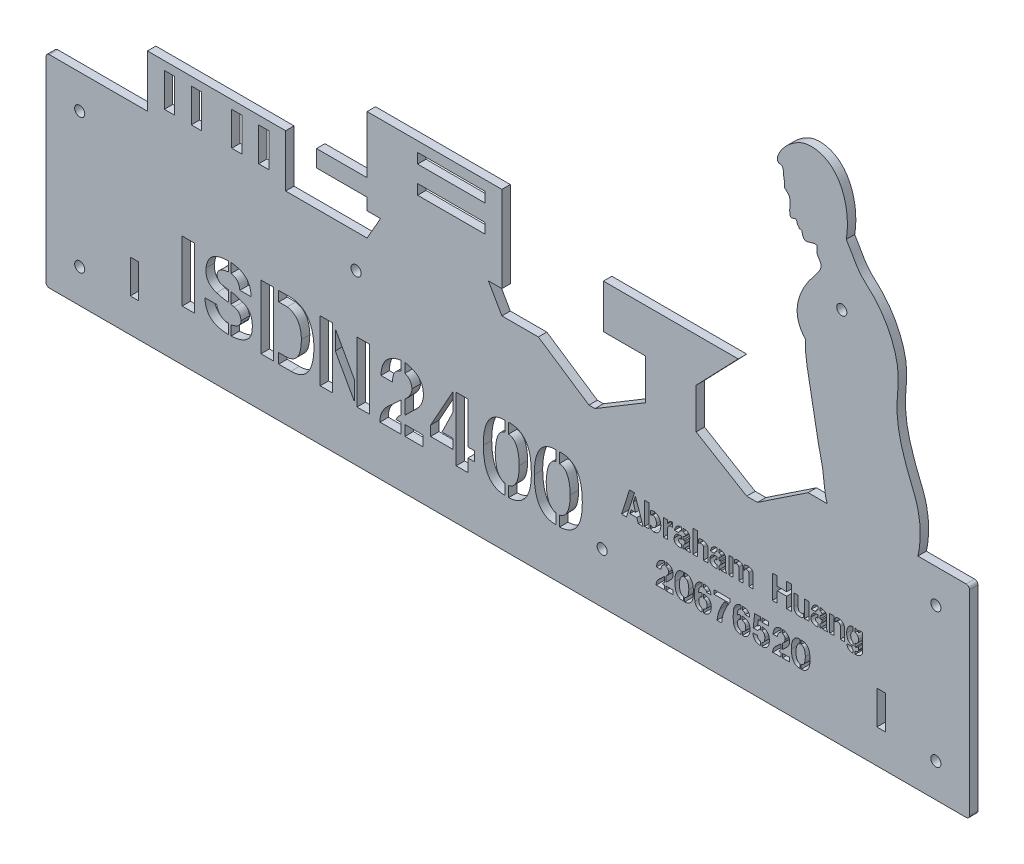
from build123d import *

# Parameters (mm, degrees)
SKETCH_1_W           = 300
SKETCH_1_H           = 200
SKETCH_1_R           = 1.5
EXTRUDE_1_DEPTH      = 2.5
SKETCH_2_R           = 1.5
CUT_EXTRUDE_1_DEPTH  = 318.657441279
SKETCH_3_R           = 2
CUT_EXTRUDE_2_DEPTH  = 318.657441279
SKETCH_4_W           = 3
SKETCH_4_H           = 10
CUT_EXTRUDE_3_DEPTH  = 318.657441279
CUT_EXTRUDE_4_DEPTH  = 10
SKETCH_12_W          = 20
SKETCH_12_H          = 3
CUT_EXTRUDE_8_DEPTH  = 298.144385253
SKETCH_18_R          = 1.5
EXTRUDE_5_DEPTH      = 2.5
CUT_EXTRUDE_5_DEPTH  = 298.144385253
EXTRUDE_2_DEPTH      = 2.5
CUT_EXTRUDE_6_DEPTH  = 298.144385253
CUT_EXTRUDE_7_DEPTH  = 298.144385253
SKETCH_10_W          = 15
SKETCH_10_H          = 5
EXTRUDE_3_DEPTH      = 2.5
SKETCH_11_R          = 2
SKETCH_11_R_2        = 1.5
EXTRUDE_4_DEPTH      = 2.5
SKETCH_13_W          = 16
SKETCH_13_H          = 60
CUT_EXTRUDE_9_DEPTH  = 298.144385253
SKETCH_19_W          = 10
SKETCH_19_H          = 60
CUT_EXTRUDE_14_DEPTH = 283.118389483
SKETCH_14_R          = 1.5
CUT_EXTRUDE_10_DEPTH = 283.118389483
SKETCH_15_W          = 2.5
SKETCH_15_H          = 10
CUT_EXTRUDE_11_DEPTH = 283.118389483
FILLET_1_R           = 1
SKETCH_16_W          = 3.609234716
SKETCH_16_H          = 18
SKETCH_16_W_2        = 3.713125267
SKETCH_16_H_2        = 18.946558359
SKETCH_16_W_3        = 3.690038478
SKETCH_16_W_4        = 5.363830697
SKETCH_16_H_3        = 3.039760582
CUT_EXTRUDE_12_DEPTH = 283.118389483
SKETCH_17_W          = 1.303334758
SKETCH_17_H          = 6.696237708
SKETCH_17_W_2        = 1.312312954
SKETCH_17_W_3        = 1.322787516
SKETCH_17_H_2        = 5.0696879
SKETCH_17_W_4        = 1.271911073
SKETCH_17_H_3        = 5.060709705
SKETCH_17_W_5        = 1.282385635
SKETCH_17_W_6        = 2.08593416
SKETCH_17_H_4        = 1.182129115
SKETCH_17_W_7        = 1.98567764
SKETCH_17_H_5        = 1.150705429
CUT_EXTRUDE_13_DEPTH = 283.118389483
SKETCH_20_W          = 0.568169596
SKETCH_20_H          = 6.048124058
SKETCH_20_H_2        = 6.048124059
SKETCH_20_W_2        = 0.62877805
SKETCH_20_H_3        = 7.576056771
SKETCH_20_W_3        = 0.477291657
SKETCH_20_H_4        = 8.489299578
EXTRUDE_6_DEPTH      = 2.5


with BuildPart() as part:
    # 草图1 → 凸台-拉伸1 (new body)
    with BuildSketch(Plane.XY):
        with Locations((-130, 50)):
            Rectangle(SKETCH_1_W, SKETCH_1_H)
        with Locations((-9.48275115, 19.751663277)):
            Circle(SKETCH_1_R, mode=Mode.SUBTRACT)
        with Locations((-27.916084483, 61.98499661)):
            Circle(SKETCH_1_R, mode=Mode.SUBTRACT)
        with Locations((-5.749417816, 42.751663277)):
            Circle(SKETCH_1_R, mode=Mode.SUBTRACT)
    extrude(amount=EXTRUDE_1_DEPTH)

    # 草图2 → 切除-拉伸1 (cut, through all)
    with BuildSketch(Plane.XY.offset(2.5)):
        with Locations((-63.75, 0)):
            Circle(SKETCH_2_R)
    extrude(amount=-CUT_EXTRUDE_1_DEPTH, mode=Mode.SUBTRACT)

    # 草图3 → 切除-拉伸2 (cut, through all)
    with BuildSketch(Plane.XY.offset(2.5)):
        with Locations((-133.403158579, -15)):
            Circle(SKETCH_3_R)
        with Locations((-213.403158579, -10)):
            Circle(SKETCH_3_R)
    extrude(amount=-CUT_EXTRUDE_2_DEPTH, mode=Mode.SUBTRACT)

    # 草图4 → 切除-拉伸3 (cut, through all)
    with BuildSketch(Plane.XY.offset(2.5)):
        with Locations((-219.403158579, 18)):
            Rectangle(SKETCH_4_W, SKETCH_4_H)
        with Locations((-227.403158579, 18)):
            Rectangle(SKETCH_4_W, SKETCH_4_H)
        with Locations((-207.403158579, 18)):
            Rectangle(SKETCH_4_W, SKETCH_4_H)
        with Locations((-199.403158579, 18)):
            Rectangle(SKETCH_4_W, SKETCH_4_H)
    extrude(amount=-CUT_EXTRUDE_3_DEPTH, mode=Mode.SUBTRACT)

    # 草图5 → 切除-拉伸4-人 (cut)
    with BuildSketch(Plane.XY.offset(2.5)):
        with BuildLine():
            Line((-280, 150), (-280, 42.5))
            Line((-280, 42.5), (-128.75, 42.5))
            Line((-128.75, 42.5), (-128.75, 10))
            Line((-128.75, 10), (-32.214611643, 10))
            add(Edge.make_bspline(
                [(-38.752031955, 49.147053584), (-38.895559541, 44.356355722), (-36.848888879, 36.737937413), (-35.454844721, 25.78337373), (-33.14551035, 17.999261722), (-33.002057772, 11.951246007), (-32.214611643, 10)],
                knots=[0, 0, 0, 0, 0.308240807, 0.511644167, 0.709108681, 0.855402211, 0.855402211, 0.855402211, 0.855402211], degree=3))
            add(Edge.make_bspline(
                [(-35.241116298, 74.807214634), (-35.268914393, 74.153975951), (-35.570103075, 72.540655065), (-33.325851828, 70.478189871), (-35.135023063, 67.709013911), (-39.959669249, 62.064786926), (-43.458763809, 54.134606099), (-38.752031955, 49.147053584)],
                knots=[0.017680517, 0.017680517, 0.017680517, 0.017680517, 0.086993237, 0.176837149, 0.283183545, 0.373621409, 1, 1, 1, 1], degree=3))
            add(Edge.make_bspline(
                [(-35.241116298, 74.807214634), (-35.890690901, 75.202516424), (-36.978463223, 74.579989734), (-39.132196474, 74.158904638), (-39.633273074, 75.486283479), (-39.748488736, 76.65522901), (-40.702794344, 76.411195616), (-40.610937532, 77.113209442), (-41.028257999, 77.082177411), (-41.318508045, 78.55414076), (-41.818601632, 78.56309284), (-42.681796182, 78.088831079), (-43.310611461, 78.293293042), (-43.371414761, 79.742182398), (-43.359729761, 80.248577876), (-43.131740362, 83.41487138), (-44.26059552, 84.246761978), (-45.078796174, 84.990715074), (-44.814885092, 85.529020475), (-44.872045073, 86.616702526), (-45.35715758, 87.956001843), (-45.125141482, 90.177884938), (-46.680104039, 90.333941903), (-47.482351389, 91.350815371), (-45.629002864, 94.7066703), (-43.04843592, 97.185207333), (-38.782239247, 99.954882069), (-27.773525037, 98.561028937), (-25.418859594, 87.356302184), (-26.587315822, 80.737792656)],
                knots=[0, 0, 0, 0, 0.043192732, 0.06409708, 0.09120207, 0.100428521, 0.112327222, 0.119288127, 0.126513334, 0.131604577, 0.149013049, 0.160157681, 0.174274215, 0.18889404, 0.224193072, 0.256573659, 0.280333772, 0.294839023, 0.303662431, 0.313258986, 0.34403195, 0.378991569, 0.39315276, 0.405387097, 0.468198731, 0.523468061, 0.594118428, 0.700759546, 0.999216099, 0.999216099, 0.999216099, 0.999216099], degree=3))
            add(Edge.make_bspline(
                [(-26.587315822, 80.737792656), (-24.95719335, 78.335637183), (-23.420207597, 74.447923828), (-17.304211112, 69.469474252), (-12.995484132, 62.935187198), (-10.564852393, 53.527514229), (-12.128168605, 44.533628714), (-10.542563825, 36.472564057), (-8.49125282, 30.475085659), (-6.880366215, 26.726308469), (-4.428795129, 20.344732823), (-4.290279041, 14.428324958), (-5.335957256, 10)],
                knots=[0.009067437, 0.009067437, 0.009067437, 0.009067437, 0.120883108, 0.161371443, 0.308805554, 0.411577695, 0.525839845, 0.652385907, 0.720933238, 0.768716708, 0.808519916, 0.982689731, 0.982689731, 0.982689731, 0.982689731], degree=3))
            Line((-5.335957256, 10), (20, 10))
            Line((20, 10), (20, 150))
            Line((20, 150), (-280, 150))
        make_face()
    extrude(amount=-CUT_EXTRUDE_4_DEPTH, mode=Mode.SUBTRACT)

    # 草图12 → 切除-拉伸8 (cut, through all)
    with BuildSketch(Plane.XY.offset(2.5)):
        with Locations((-143.75, 30)):
            Rectangle(SKETCH_12_W, SKETCH_12_H)
        with Locations((-143.75, 38)):
            Rectangle(SKETCH_12_W, SKETCH_12_H)
    extrude(amount=-CUT_EXTRUDE_8_DEPTH, mode=Mode.SUBTRACT)

    # 草图18 → 凸台-拉伸5 (add)
    with BuildSketch(Plane.XY.offset(2.5)):
        with Locations((-63.75, 0)):
            Circle(SKETCH_18_R)
    extrude(amount=-EXTRUDE_5_DEPTH)

    # 草图7 → 切除-拉伸5 (cut, through all)
    with BuildSketch(Plane.XY.offset(2.5)):
        Polygon((-117.916084483, 10), (-102.916084483, 0), (-52.916084483, 0), (-37.916084483, 10), align=None)
    extrude(amount=-CUT_EXTRUDE_5_DEPTH, mode=Mode.SUBTRACT)

    # 草图6 → 凸台-拉伸2 (add)
    with BuildSketch(Plane.XY):
        Polygon((-101.128293069, 0), (-86.128293069, 9), (-86.128293069, 21), (-98.628293069, 21), (-98.628293069, 34), (-58.628293069, 34), (-71.128293069, 21), (-71.128293069, 9), (-56.128293069, 0), align=None)
    extrude(amount=EXTRUDE_2_DEPTH)

    # 草图8 → 切除-拉伸6 (cut, through all)
    with BuildSketch(Plane.XY.offset(2.5)):
        Polygon((-168.75, 42.5), (-168.75, 10), (-192.903158579, 10), (-192.903158579, 25.5), (-233.903158579, 25.5), (-233.903158579, 10), (-280, 10), (-280, 42.5), align=None)
    extrude(amount=-CUT_EXTRUDE_6_DEPTH, mode=Mode.SUBTRACT)

    # 草图9 → 切除-拉伸7 (cut, through all)
    with BuildSketch(Plane.XY.offset(2.5)):
        Polygon((-168.75, 17), (-164.75, 17), (-168.75, 10), align=None)
        Polygon((-132.75, 17), (-128.75, 10), (-128.75, 17), align=None)
    extrude(amount=-CUT_EXTRUDE_7_DEPTH, mode=Mode.SUBTRACT)

    # 草图10 → 凸台-拉伸3 (add)
    with BuildSketch(Plane.XY.offset(2.5)):
        with Locations((-176.25, 23)):
            Rectangle(SKETCH_10_W, SKETCH_10_H)
    extrude(amount=-EXTRUDE_3_DEPTH)

    # 草图11 → 凸台-拉伸4 (add)
    with BuildSketch(Plane.XY.offset(2.5)):
        with Locations((-213.403158579, -10)):
            Circle(SKETCH_11_R)
        with Locations((-133.403158579, -15)):
            Circle(SKETCH_11_R)
        with Locations((-9.48275115, 19.751663277)):
            Circle(SKETCH_11_R_2)
    extrude(amount=-EXTRUDE_4_DEPTH)

    # 草图13 → 切除-拉伸9 (cut, through all)
    with BuildSketch(Plane.XY.offset(2.5)):
        with Locations((-272, -20)):
            Rectangle(SKETCH_13_W, SKETCH_13_H)
    extrude(amount=-CUT_EXTRUDE_9_DEPTH, mode=Mode.SUBTRACT)

    # 草图19 → 切除-拉伸14 (cut, through all)
    with BuildSketch(Plane.XY.offset(2.5)):
        with Locations((15, -20)):
            Rectangle(SKETCH_19_W, SKETCH_19_H)
    extrude(amount=-CUT_EXTRUDE_14_DEPTH, mode=Mode.SUBTRACT)

    # 草图14 → 切除-拉伸10 (cut, through all)
    with BuildSketch(Plane.XY.offset(2.5)):
        with Locations((-254, 0)):
            Circle(SKETCH_14_R)
        with Locations((-254, -40)):
            Circle(SKETCH_14_R)
        with Locations((0, -40)):
            Circle(SKETCH_14_R)
        Circle(SKETCH_14_R)
        with Locations((-172, 0)):
            Circle(SKETCH_14_R)
        with Locations((-99, -35)):
            Circle(SKETCH_14_R)
    extrude(amount=-CUT_EXTRUDE_10_DEPTH, mode=Mode.SUBTRACT)

    # 草图15 → 切除-拉伸11 (cut, through all)
    with BuildSketch(Plane.XY.offset(2.5)):
        with Locations((-237.75, -35)):
            Rectangle(SKETCH_15_W, SKETCH_15_H)
        with Locations((-16.25, -35)):
            Rectangle(SKETCH_15_W, SKETCH_15_H)
    extrude(amount=-CUT_EXTRUDE_11_DEPTH, mode=Mode.SUBTRACT)

    # 圆角1
    fillet_1_edges = [part.edges().sort_by_distance(p)[0] for p in [
        (-264, 10, 1.25),
        (-264, -50, 1.25),
        (10, -50, 1.25),
        (10, 10, 1.25),
    ]]
    fillet(fillet_1_edges, radius=FILLET_1_R)

    # 草图16 → 切除-拉伸12 (cut, through all)
    with BuildSketch(Plane.XY.offset(2.5)):
        with Locations((-221.796550036, -25.91133829)):
            Rectangle(SKETCH_16_W, SKETCH_16_H)
        with BuildLine():
            add(Edge.make_bspline(
                [(-209.896849309, -32.441051843), (-210.011082299, -32.435977958), (-210.233721066, -32.426089014), (-210.559800303, -32.389100916), (-210.868518276, -32.322893712), (-211.160160063, -32.234133512), (-211.43751034, -32.127356998), (-211.695461071, -31.990941453), (-211.939437872, -31.833130184), (-212.165613563, -31.65073976), (-212.3808938, -31.451173683), (-212.57209855, -31.221265873), (-212.750087702, -30.970606595), (-212.910120861, -30.696734215), (-213.059441418, -30.402759521), (-213.183739335, -30.08201639), (-213.296594745, -29.739278748), (-213.356253273, -29.500483177), (-213.386802281, -29.378204472)],
                knots=[0, 0, 0, 0, 1.081541665, 2.107912116, 3.100227153, 4.063637973, 4.989650665, 5.906797966, 6.818794522, 7.734013691, 8.652364019, 9.590694611, 10.556851936, 11.557734305, 12.588684234, 13.672401494, 14.808119729, 16, 16, 16, 16], degree=3))
            Line((-213.386802281, -29.378204472), (-216.842125068, -29.378204472))
            add(Edge.make_bspline(
                [(-216.842125068, -29.378204472), (-216.830601932, -29.617090684), (-216.808210986, -30.081277546), (-216.711368102, -30.754925961), (-216.563132362, -31.382709387), (-216.361122344, -31.96493667), (-216.113341946, -32.505260393), (-215.801708761, -32.994037132), (-215.446501558, -33.442536252), (-215.034838035, -33.841705575), (-214.568668772, -34.191661176), (-214.055821134, -34.502136758), (-213.487331964, -34.758763707), (-212.86961927, -34.974841861), (-212.198350398, -35.142669763), (-211.476383636, -35.262708806), (-210.704256297, -35.347211377), (-210.171565254, -35.359197218), (-209.896849309, -35.365378478)],
                knots=[0, 0, 0, 0, 1.101430997, 2.140223135, 3.130640524, 4.068800979, 4.975578942, 5.862557957, 6.732844266, 7.606254772, 8.496220918, 9.413394999, 10.362674972, 11.364416193, 12.425015239, 13.546133459, 14.734507976, 16, 16, 16, 16], degree=3))
            Line((-209.896849309, -35.365378478), (-209.896849309, -32.441051843))
        make_face()
        with BuildLine():
            Line((-209.127289668, -27.184959496), (-208.169187915, -27.431218581))
            add(Edge.make_bspline(
                [(-208.169187915, -27.431218581), (-208.02256352, -27.467218899), (-207.737990646, -27.537089358), (-207.350395863, -27.722306469), (-207.010263961, -27.95546618), (-206.726185194, -28.248903744), (-206.496088125, -28.597526428), (-206.324235419, -29.000880449), (-206.199801556, -29.45542776), (-206.161424461, -29.778888244), (-206.141398262, -29.947678606)],
                knots=[0, 0, 0, 0, 1.032119431, 2.003167286, 2.924715266, 3.844501604, 4.782908314, 5.770712865, 6.836698135, 8, 8, 8, 8], degree=3))
            add(Edge.make_bspline(
                [(-206.141398262, -29.947678606), (-206.151875005, -30.108064192), (-206.172201883, -30.419242799), (-206.327697462, -30.858464612), (-206.564952629, -31.252685861), (-206.904151621, -31.592339477), (-207.330471512, -31.881989839), (-207.847541916, -32.116502536), (-208.447973957, -32.315819329), (-208.884820511, -32.397744546), (-209.115746274, -32.441051843)],
                knots=[0, 0, 0, 0, 0.903286726, 1.752548426, 2.600451702, 3.480884551, 4.438622935, 5.494265168, 6.675418813, 8, 8, 8, 8], degree=3))
            Line((-209.115746274, -32.441051843), (-209.115746274, -35.365378478))
            add(Edge.make_bspline(
                [(-209.115746274, -35.365378478), (-208.875674541, -35.34577498), (-208.408498361, -35.30762685), (-207.731424109, -35.215600226), (-207.097019976, -35.094786), (-206.508118326, -34.935137619), (-205.960041608, -34.753380186), (-205.456825924, -34.536911666), (-204.996409549, -34.290845598), (-204.580180407, -34.013824876), (-204.205232725, -33.708008995), (-203.878492634, -33.368666853), (-203.59291536, -32.999192816), (-203.355847773, -32.597318347), (-203.156425964, -32.167760669), (-203.008223248, -31.705943268), (-202.898319557, -31.215170949), (-202.862268327, -30.875514591), (-202.843835201, -30.701847054)],
                knots=[0, 0, 0, 0, 1.336264232, 2.600351199, 3.78945896, 4.916692332, 5.983400731, 6.990724353, 7.952288396, 8.876002732, 9.760764016, 10.631446688, 11.484055816, 12.345705022, 13.215019725, 14.106197263, 15.03169174, 16, 16, 16, 16], degree=3))
            add(Edge.make_bspline(
                [(-202.843835201, -30.701847054), (-202.82766923, -30.53523824), (-202.796006479, -30.208917371), (-202.784301797, -29.72844525), (-202.784318987, -29.268663008), (-202.816164899, -28.830565175), (-202.869594796, -28.412961906), (-202.945554198, -28.016749702), (-203.046584855, -27.641582218), (-203.167185884, -27.286051687), (-203.320744246, -26.955317312), (-203.487207898, -26.640492424), (-203.686540471, -26.35161009), (-203.904989015, -26.081173082), (-204.149993778, -25.832587733), (-204.418921458, -25.607435629), (-204.710007618, -25.399530744), (-204.919174191, -25.28223041), (-205.025536783, -25.222582411)],
                knots=[0, 0, 0, 0, 1.275738218, 2.498667344, 3.662341329, 4.779823541, 5.844729788, 6.870719406, 7.852709217, 8.805190321, 9.728565962, 10.629933347, 11.516810328, 12.399526716, 13.277681792, 14.172875355, 15.070894982, 16, 16, 16, 16], degree=3))
            add(Edge.make_bspline(
                [(-205.025536783, -25.222582411), (-205.239127902, -25.132575879), (-205.65249861, -24.958382943), (-206.260384977, -24.730855783), (-206.827942459, -24.525026956), (-207.357499636, -24.345069912), (-207.854352327, -24.204827486), (-208.31170196, -24.087497149), (-208.731348769, -24.00004418), (-209.000065314, -23.965375268), (-209.127289668, -23.948961206)],
                knots=[0, 0, 0, 0, 1.291198861, 2.498904388, 3.615527432, 4.654991241, 5.613968697, 6.490925993, 7.285526069, 8, 8, 8, 8], degree=3))
            Line((-209.127289668, -23.948961206), (-209.127289668, -27.184959496))
        make_face()
        with BuildLine():
            add(Edge.make_bspline(
                [(-203.16705025, -22.286712381), (-203.169971237, -22.073622057), (-203.175669732, -21.657908361), (-203.24231333, -21.052930434), (-203.351913323, -20.482877009), (-203.513747371, -19.950458455), (-203.72269048, -19.454013914), (-203.976473454, -18.993506996), (-204.280007676, -18.571223718), (-204.627269751, -18.182666115), (-205.027852498, -17.836153898), (-205.472893228, -17.523550925), (-205.964325466, -17.244749193), (-206.505112617, -17.007307485), (-207.091789795, -16.80905638), (-207.724204119, -16.64304737), (-208.402834157, -16.511828894), (-208.874161743, -16.457969688), (-209.115746274, -16.430363514)],
                knots=[0, 0, 0, 0, 1.090277512, 2.127000815, 3.11064997, 4.057643954, 4.969677273, 5.863018473, 6.742943482, 7.62616845, 8.524129166, 9.447574206, 10.40599084, 11.411180255, 12.465832364, 13.572529549, 14.755771301, 16, 16, 16, 16], degree=3))
            Line((-209.115746274, -16.430363514), (-209.115746274, -19.300820975))
            add(Edge.make_bspline(
                [(-209.115746274, -19.300820975), (-208.929683784, -19.330723263), (-208.570674535, -19.388419996), (-208.070539112, -19.57004883), (-207.636661147, -19.833329683), (-207.268072444, -20.174227613), (-206.968171086, -20.595268794), (-206.737977317, -21.092628646), (-206.571997904, -21.663701508), (-206.519179347, -22.072732374), (-206.491547898, -22.286712381)],
                knots=[0, 0, 0, 0, 1.035444468, 1.997899424, 2.907008058, 3.811060859, 4.741537715, 5.732958946, 6.814022359, 8, 8, 8, 8], degree=3))
            Line((-206.491547898, -22.286712381), (-203.16705025, -22.286712381))
        make_face()
        with BuildLine():
            add(Edge.make_bspline(
                [(-209.896849309, -16.430363514), (-210.143228668, -16.436553537), (-210.622739219, -16.448600735), (-211.319932455, -16.512365071), (-211.973181709, -16.623054755), (-212.585208429, -16.759264984), (-213.15057685, -16.948942565), (-213.676832984, -17.16370983), (-214.156541527, -17.428252432), (-214.594178675, -17.729133178), (-214.989302268, -18.068320148), (-215.337872599, -18.449093176), (-215.643503629, -18.867272316), (-215.906951791, -19.325126907), (-216.125383724, -19.821960428), (-216.299126212, -20.356861633), (-216.425810527, -20.93074156), (-216.477122015, -21.328117077), (-216.503518826, -21.532543933)],
                knots=[0, 0, 0, 0, 1.2678559, 2.467537386, 3.597976775, 4.675257356, 5.689449335, 6.662554843, 7.595798877, 8.501887044, 9.390872406, 10.268915689, 11.151929279, 12.050658305, 12.98133238, 13.939192708, 14.939833134, 16, 16, 16, 16], degree=3))
            add(Edge.make_bspline(
                [(-216.503518826, -21.532543933), (-216.517358222, -21.685058566), (-216.544418279, -21.983269183), (-216.545484038, -22.422922072), (-216.526878498, -22.841427889), (-216.466548338, -23.238804835), (-216.380369176, -23.615476665), (-216.258545697, -23.971028244), (-216.114961045, -24.308823592), (-215.930961726, -24.621831561), (-215.719542548, -24.914217699), (-215.478433035, -25.18745023), (-215.205130611, -25.436169347), (-214.900287612, -25.665210742), (-214.568464075, -25.876516504), (-214.20135808, -26.061468389), (-213.806240151, -26.226528837), (-213.528548758, -26.318455086), (-213.386802281, -26.365378478)],
                knots=[0, 0, 0, 0, 1.157383638, 2.263022786, 3.321728647, 4.321586016, 5.297835616, 6.239362071, 7.160079859, 8.068301078, 8.978126062, 9.885000003, 10.818550889, 11.767044337, 12.765254144, 13.788863963, 14.871334317, 16, 16, 16, 16], degree=3))
            add(Edge.make_bspline(
                [(-213.386802281, -26.365378478), (-213.212562821, -26.418607205), (-212.874040173, -26.5220231), (-212.377011851, -26.662274088), (-211.903035815, -26.777234319), (-211.453914408, -26.873141904), (-211.02969323, -26.952620582), (-210.6300747, -27.005065134), (-210.255341202, -27.042146699), (-210.013641705, -27.05022892), (-209.896849309, -27.054134357)],
                knots=[0, 0, 0, 0, 1.225235341, 2.380459126, 3.472513928, 4.504494983, 5.468870607, 6.374028452, 7.214309027, 8, 8, 8, 8], degree=3))
            Line((-209.896849309, -27.054134357), (-209.896849309, -23.818136067))
            Line((-209.896849309, -23.818136067), (-211.285904461, -23.610354964))
            add(Edge.make_bspline(
                [(-211.285904461, -23.610354964), (-211.439551457, -23.585309328), (-211.72990344, -23.537979733), (-212.13058456, -23.401697428), (-212.472636409, -23.217922946), (-212.751252067, -22.977444465), (-212.973323952, -22.692691361), (-213.123216, -22.354342451), (-213.217685578, -21.972481067), (-213.227673984, -21.701169101), (-213.232890352, -21.559478521)],
                knots=[0, 0, 0, 0, 1.184309266, 2.23802973, 3.208939335, 4.123591262, 5.022607861, 5.936424298, 6.922313519, 8, 8, 8, 8], degree=3))
            add(Edge.make_bspline(
                [(-213.232890352, -21.559478521), (-213.208122425, -21.399814035), (-213.159772056, -21.088127206), (-212.963990267, -20.657395723), (-212.672842013, -20.286432626), (-212.291954424, -19.971823516), (-211.818976944, -19.717711869), (-211.257960089, -19.520711856), (-210.608100308, -19.375620812), (-210.142551806, -19.326660667), (-209.896849309, -19.300820975)],
                knots=[0, 0, 0, 0, 0.876798459, 1.711630044, 2.543035072, 3.425823873, 4.382520999, 5.452026841, 6.6552564, 8, 8, 8, 8], degree=3))
            Line((-209.896849309, -19.300820975), (-209.896849309, -16.430363514))
        make_face()
        with Locations((-198.349222118, -25.995989851)):
            Rectangle(SKETCH_16_W_2, SKETCH_16_H_2)
        with BuildLine():
            Line((-194.961235799, -35.507747012), (-191.325066496, -35.507747012))
            add(Edge.make_bspline(
                [(-191.325066496, -35.507747012), (-191.047622999, -35.502318259), (-190.508100039, -35.491761381), (-189.725261926, -35.374802216), (-188.998014753, -35.177263975), (-188.319496134, -34.909912521), (-187.700151466, -34.55114021), (-187.133457245, -34.116745912), (-186.620777945, -33.603460116), (-186.166224041, -33.009403328), (-185.764122226, -32.33799205), (-185.419577173, -31.587431202), (-185.127238439, -30.759099089), (-184.891550117, -29.852539723), (-184.706353486, -28.867894916), (-184.585030133, -27.804372468), (-184.505176861, -26.662891866), (-184.498614718, -25.875573829), (-184.495224683, -25.468841496)],
                knots=[0, 0, 0, 0, 0.963980726, 1.874578932, 2.743169707, 3.579467905, 4.402441226, 5.222946565, 6.055336583, 6.916894305, 7.816961837, 8.770563553, 9.78317987, 10.866901506, 12.023916578, 13.263367512, 14.586242326, 16, 16, 16, 16], degree=3))
            add(Edge.make_bspline(
                [(-184.495224683, -25.468841496), (-184.520100394, -25.133769539), (-184.568548601, -24.481179705), (-184.694748221, -23.533987168), (-184.868081756, -22.646381129), (-185.081458642, -21.817907813), (-185.339769536, -21.048880395), (-185.637494762, -20.337635992), (-185.985021583, -19.688996555), (-186.37438304, -19.098168437), (-186.811959967, -18.57111222), (-187.284339741, -18.094695992), (-187.811367401, -17.691354898), (-188.373274023, -17.335565059), (-188.987034121, -17.052733635), (-189.640459622, -16.825811651), (-190.33580105, -16.652954469), (-190.817591665, -16.592191705), (-191.063416218, -16.561188653)],
                knots=[0, 0, 0, 0, 1.319821239, 2.570498372, 3.751423221, 4.870936382, 5.928989028, 6.936016362, 7.89637636, 8.815961506, 9.710819872, 10.583775025, 11.445562471, 12.312446646, 13.191589707, 14.093569974, 15.027280121, 16, 16, 16, 16], degree=3))
            Line((-191.063416218, -16.561188653), (-194.949692405, -16.561188653))
            Line((-194.949692405, -16.561188653), (-194.949692405, -19.520145473))
            Line((-194.949692405, -19.520145473), (-192.440927975, -19.520145473))
            add(Edge.make_bspline(
                [(-192.440927975, -19.520145473), (-192.274673685, -19.554158672), (-191.948564899, -19.620875766), (-191.482792579, -19.772926905), (-191.046978234, -19.958528556), (-190.641623567, -20.180373033), (-190.269545594, -20.446267343), (-189.924810597, -20.745088778), (-189.617649739, -21.088669455), (-189.333425955, -21.461549019), (-189.087682296, -21.877347999), (-188.872764538, -22.328502924), (-188.687524606, -22.816222479), (-188.534359155, -23.34130394), (-188.411835441, -23.904532417), (-188.32070081, -24.506021544), (-188.258573597, -25.144452136), (-188.243173857, -25.582853696), (-188.235284538, -25.807447738)],
                knots=[0, 0, 0, 0, 0.98044399, 1.923146757, 2.826715524, 3.716208529, 4.588567588, 5.466111358, 6.347999199, 7.248214741, 8.172748117, 9.134592399, 10.134417809, 11.185609797, 12.293939098, 13.464331594, 14.700971739, 16, 16, 16, 16], degree=3))
            add(Edge.make_bspline(
                [(-188.235284538, -25.807447738), (-188.239077758, -26.073036612), (-188.246452454, -26.589388741), (-188.300340783, -27.33827367), (-188.38809678, -28.037159055), (-188.508302461, -28.686126676), (-188.671777024, -29.283053498), (-188.860768914, -29.833800967), (-189.092506953, -30.33021234), (-189.354978417, -30.779691857), (-189.656120007, -31.177242637), (-189.991212971, -31.527521376), (-190.366322746, -31.821436746), (-190.771137986, -32.071454874), (-191.215789086, -32.26225286), (-191.692090399, -32.411086253), (-192.205519803, -32.502503797), (-192.559862016, -32.522945869), (-192.741056235, -32.533399)],
                knots=[0, 0, 0, 0, 1.396328444, 2.714711479, 3.945114761, 5.098405143, 6.181353718, 7.196570677, 8.155985813, 9.056929254, 9.928209324, 10.772342994, 11.598039353, 12.427280493, 13.266741228, 14.134883989, 15.046265935, 16, 16, 16, 16], degree=3))
            Line((-192.741056235, -32.533399), (-194.961235799, -32.533399))
            Line((-194.961235799, -32.533399), (-194.961235799, -35.507747012))
        make_face()
        with Locations((-180.804801426, -25.91133829)):
            Rectangle(SKETCH_16_W_3, SKETCH_16_H)
        Polygon((-178.182526949, -23.714245515), (-172.518567992, -33.872432775), (-172.518567992, -28.208473818), (-178.182526949, -17.950243805), align=None)
        with Locations((-169.896293516, -25.91133829)):
            Rectangle(SKETCH_16_W_3, SKETCH_16_H)
        with BuildLine():
            add(Edge.make_bspline(
                [(-158.625707796, -16.35340755), (-158.862357401, -16.395115196), (-159.324863414, -16.476628271), (-159.991805526, -16.649563643), (-160.613124333, -16.864997795), (-161.189821326, -17.119714736), (-161.722656396, -17.411592014), (-162.212083048, -17.744213325), (-162.654103573, -18.118348801), (-163.056708248, -18.529586031), (-163.408796088, -18.984369824), (-163.719790831, -19.477703285), (-163.985198901, -20.010006204), (-164.204916274, -20.582220456), (-164.376513713, -21.193288798), (-164.508047982, -21.842534468), (-164.592059504, -22.532262507), (-164.613463453, -23.006028869), (-164.624425196, -23.248661933)],
                knots=[0, 0, 0, 0, 1.141291356, 2.230530302, 3.269220259, 4.262222097, 5.222200438, 6.151760379, 7.068489867, 7.969099464, 8.880833557, 9.795434202, 10.735578764, 11.701975471, 12.703021258, 13.747468341, 14.846396238, 16, 16, 16, 16], degree=3))
            Line((-164.624425196, -23.248661933), (-161.169102409, -23.248661933))
            add(Edge.make_bspline(
                [(-161.169102409, -23.248661933), (-161.173331223, -23.112716676), (-161.181551965, -22.848441458), (-161.165980411, -22.46150661), (-161.126868307, -22.095502705), (-161.070624239, -21.747935362), (-160.990616742, -21.420731712), (-160.885408676, -21.113343687), (-160.759235738, -20.826310911), (-160.613413724, -20.558236044), (-160.442312059, -20.313626253), (-160.247334236, -20.089839939), (-160.034861349, -19.880094125), (-159.791110507, -19.70138815), (-159.534479164, -19.53252456), (-159.250502051, -19.391632773), (-158.946985608, -19.267756103), (-158.734027105, -19.202955861), (-158.625707796, -19.169995836)],
                knots=[0, 0, 0, 0, 1.23948383, 2.409535034, 3.526331796, 4.593050306, 5.616678212, 6.592732781, 7.550694994, 8.471629197, 9.370024889, 10.265296247, 11.1748056, 12.084390091, 13.015141768, 13.971961849, 14.968457755, 16, 16, 16, 16], degree=3))
            Line((-158.625707796, -19.169995836), (-158.625707796, -16.35340755))
        make_face()
        with BuildLine():
            Line((-157.521389711, -29.924591817), (-154.71634482, -27.158024908))
            add(Edge.make_bspline(
                [(-154.71634482, -27.158024908), (-154.483384294, -26.95249795), (-154.030847883, -26.553252492), (-153.445383965, -25.888720339), (-152.961588297, -25.196159734), (-152.568594463, -24.477890454), (-152.292403625, -23.723107861), (-152.10994329, -22.944448046), (-152.023704954, -22.135497145), (-152.053775771, -21.590315245), (-152.069059656, -21.313219436)],
                knots=[0, 0, 0, 0, 1.113976299, 2.1639496, 3.168809745, 4.140771598, 5.093183028, 6.043256155, 7.005459426, 8, 8, 8, 8], degree=3))
            add(Edge.make_bspline(
                [(-152.069059656, -21.313219436), (-152.082755142, -21.147387027), (-152.109668507, -20.82150535), (-152.200389968, -20.346589898), (-152.324838467, -19.894330226), (-152.496211284, -19.470231388), (-152.7025066, -19.069943479), (-152.941960583, -18.690592026), (-153.233303144, -18.344923361), (-153.551208139, -18.01381664), (-153.915538598, -17.71431057), (-154.31786978, -17.442048932), (-154.755548604, -17.189338594), (-155.233970441, -16.964629055), (-155.749175763, -16.758239697), (-156.307094023, -16.589819766), (-156.898852574, -16.431921341), (-157.310440196, -16.354572758), (-157.521389711, -16.314929568)],
                knots=[0, 0, 0, 0, 0.988023166, 1.94159061, 2.867974731, 3.770802588, 4.65353112, 5.541343498, 6.429253985, 7.334586936, 8.265411172, 9.225019005, 10.218434839, 11.264887463, 12.36300604, 13.512691239, 14.725188635, 16, 16, 16, 16], degree=3))
            Line((-157.521389711, -16.314929568), (-157.521389711, -19.131517854))
            add(Edge.make_bspline(
                [(-157.521389711, -19.131517854), (-157.36909913, -19.19774071), (-157.072067219, -19.326903664), (-156.672966196, -19.589128184), (-156.325178257, -19.892632179), (-156.027083061, -20.241360375), (-155.794384838, -20.644124537), (-155.606950466, -21.08515561), (-155.479768423, -21.574263198), (-155.43820925, -21.916654684), (-155.416644093, -22.094322471)],
                knots=[0, 0, 0, 0, 1.033825601, 2.016403053, 2.962746197, 3.904720877, 4.861981465, 5.851110155, 6.884935756, 8, 8, 8, 8], degree=3))
            add(Edge.make_bspline(
                [(-155.416644093, -22.094322471), (-155.422956747, -22.206225358), (-155.435751718, -22.433038738), (-155.505890796, -22.775551789), (-155.607872701, -23.124109301), (-155.755100772, -23.477740435), (-155.933861032, -23.840063805), (-156.161543465, -24.203850994), (-156.418011292, -24.580793016), (-156.615274476, -24.82381821), (-156.717199886, -24.949388739)],
                knots=[0, 0, 0, 0, 0.840868873, 1.704337725, 2.618809252, 3.565202098, 4.577691888, 5.650015622, 6.785768761, 8, 8, 8, 8], degree=3))
            Line((-156.717199886, -24.949388739), (-157.521389711, -25.807447738))
            Line((-157.521389711, -25.807447738), (-157.521389711, -29.924591817))
        make_face()
        with Locations((-154.827930969, -33.8185636)):
            Rectangle(SKETCH_16_W_4, SKETCH_16_H_3)
        with BuildLine():
            Line((-158.625707796, -32.337161291), (-160.211000656, -32.337161291))
            add(Edge.make_bspline(
                [(-160.211000656, -32.337161291), (-160.094766724, -32.132949101), (-159.870418769, -31.738790646), (-159.475697669, -31.214361987), (-159.077893722, -30.747882053), (-158.773189142, -30.499063648), (-158.625707796, -30.378632005)],
                knots=[0, 0, 0, 0, 1.110180603, 2.14280583, 3.101091635, 4, 4, 4, 4], degree=3))
            Line((-158.625707796, -30.378632005), (-158.625707796, -26.46926903))
            add(Edge.make_bspline(
                [(-158.625707796, -26.46926903), (-158.640769102, -26.490064708), (-158.690991383, -26.559408386), (-158.819085557, -26.685357162), (-159.018851336, -26.88145605), (-159.292637743, -27.147897055), (-159.641938641, -27.480851444), (-160.065448831, -27.882162489), (-160.567187079, -28.347400049), (-160.926679001, -28.680483592), (-161.119081032, -28.858751714)],
                knots=[0, 0, 0, 0, 0.178192026, 0.594185499, 1.243120148, 2.125215673, 3.246905815, 4.595644072, 6.177970198, 8, 8, 8, 8], degree=3))
            add(Edge.make_bspline(
                [(-161.119081032, -28.858751714), (-161.281728814, -28.988318573), (-161.601525295, -29.243071668), (-162.054043987, -29.639144438), (-162.475718355, -30.036395319), (-162.863565116, -30.435555537), (-163.219761956, -30.835997798), (-163.538865241, -31.239982109), (-163.825277867, -31.645910909), (-164.079629711, -32.052497974), (-164.30002693, -32.462833873), (-164.489160821, -32.873511294), (-164.644106895, -33.286186232), (-164.763416344, -33.700733373), (-164.853522938, -34.116983761), (-164.906885785, -34.536600933), (-164.927034051, -34.957472075), (-164.915118191, -35.237136614), (-164.909162263, -35.376921873)],
                knots=[0, 0, 0, 0, 1.270310294, 2.497671711, 3.672817814, 4.808828716, 5.896883223, 6.945685018, 7.952274225, 8.930745431, 9.873842482, 10.796035912, 11.69116517, 12.564102424, 13.429373973, 14.290519739, 15.145547225, 16, 16, 16, 16], degree=3))
            Line((-164.909162263, -35.376921873), (-158.625707796, -35.376921873))
            Line((-158.625707796, -35.376921873), (-158.625707796, -32.337161291))
        make_face()
        Polygon((-142.324125923, -35.299965909), (-138.841868548, -35.299965909), (-138.841868548, -31.559906054), (-136.944904033, -31.559906054), (-136.944904033, -28.727926576), (-138.841868548, -28.727926576), (-138.841868548, -16.391885532), (-142.324125923, -16.391885532), align=None)
        Polygon((-143.309162263, -16.780513151), (-149.908136184, -28.624036024), (-149.908136184, -31.559906054), (-143.309162263, -31.559906054), (-143.309162263, -28.727926576), (-146.518225966, -28.727926576), (-143.309162263, -22.132800453), align=None)
        with BuildLine():
            Line((-126.788255893, -16.338016357), (-126.788255893, -19.404711526))
            add(Edge.make_bspline(
                [(-126.788255893, -19.404711526), (-126.663171544, -19.420373719), (-126.418342741, -19.45102948), (-126.0653002, -19.557885748), (-125.738007079, -19.713757574), (-125.430134416, -19.909986193), (-125.150970776, -20.158233726), (-124.892199474, -20.44828718), (-124.65651789, -20.784993627), (-124.450399534, -21.170608931), (-124.261595687, -21.598558646), (-124.095988073, -22.073079572), (-123.960706798, -22.595205621), (-123.840525661, -23.161122276), (-123.746073144, -23.773961475), (-123.672359061, -24.432392791), (-123.628521131, -25.137434195), (-123.613744238, -25.622704451), (-123.606126778, -25.872860308)],
                knots=[0, 0, 0, 0, 0.766646972, 1.500565519, 2.234317794, 2.96877646, 3.716040072, 4.501553437, 5.331478872, 6.21229334, 7.160003444, 8.177739987, 9.269037423, 10.442469304, 11.699634313, 13.043489992, 14.475924938, 16, 16, 16, 16], degree=3))
            add(Edge.make_bspline(
                [(-123.606126778, -25.872860308), (-123.610910094, -26.120446508), (-123.620210816, -26.601855371), (-123.660648505, -27.301756014), (-123.732690088, -27.958384604), (-123.816640428, -28.573196505), (-123.933365841, -29.144462046), (-124.070613184, -29.67293353), (-124.231787723, -30.159193067), (-124.414977799, -30.602662117), (-124.623103532, -31.002360451), (-124.856046819, -31.35839604), (-125.106511691, -31.677768372), (-125.393142343, -31.944528733), (-125.696944237, -32.172832225), (-126.023595566, -32.361407649), (-126.376747328, -32.501115233), (-126.624472121, -32.558328289), (-126.749777911, -32.587268175)],
                knots=[0, 0, 0, 0, 1.482756099, 2.883084468, 4.195999281, 5.43744608, 6.597217053, 7.685110349, 8.705147546, 9.662205999, 10.555378525, 11.398931541, 12.207350703, 12.978808729, 13.736067874, 14.479094956, 15.230685768, 16, 16, 16, 16], degree=3))
            Line((-126.749777911, -32.587268175), (-126.749777911, -35.70398472))
            add(Edge.make_bspline(
                [(-126.749777911, -35.70398472), (-126.472113263, -35.682327565), (-125.92997009, -35.640041739), (-125.146539554, -35.489739944), (-124.41866463, -35.266760638), (-123.74500497, -34.972435861), (-123.126963618, -34.605852609), (-122.562636953, -34.168096589), (-122.059478244, -33.652668135), (-121.607367621, -33.070012695), (-121.215171903, -32.413414279), (-120.874242793, -31.689745266), (-120.596969863, -30.891259969), (-120.365633358, -30.024911739), (-120.194047401, -29.086809009), (-120.083189913, -28.078714248), (-120.014116009, -26.999955266), (-120.017983437, -26.256466246), (-120.019978852, -25.872860308)],
                knots=[0, 0, 0, 0, 0.991946515, 1.936786101, 2.836060025, 3.699746567, 4.550270473, 5.390526109, 6.237345084, 7.110474391, 8.012728719, 8.957380335, 9.956336716, 11.020703748, 12.150291089, 13.351123103, 14.633302066, 16, 16, 16, 16], degree=3))
            add(Edge.make_bspline(
                [(-120.019978852, -25.872860308), (-120.022199705, -25.477692093), (-120.026494246, -24.713541537), (-120.101081111, -23.605072321), (-120.223696368, -22.575188325), (-120.406424857, -21.623251098), (-120.63072357, -20.748119642), (-120.922360142, -19.953042245), (-121.261759154, -19.233811594), (-121.660471056, -18.593116105), (-122.111380333, -18.029470871), (-122.620910317, -17.547537011), (-123.182757699, -17.142655248), (-123.80188916, -16.82174266), (-124.473439063, -16.57865987), (-125.198168236, -16.413824646), (-125.976873511, -16.328823771), (-126.5123155, -16.334890081), (-126.788255893, -16.338016357)],
                knots=[0, 0, 0, 0, 1.413178244, 2.732712046, 3.971484364, 5.120456093, 6.197613235, 7.199042918, 8.144997564, 9.037337105, 9.89209149, 10.719610085, 11.538230097, 12.361068473, 13.205717032, 14.085993525, 15.013615459, 16, 16, 16, 16], degree=3))
        make_face()
        with BuildLine():
            add(Edge.make_bspline(
                [(-127.761748839, -32.560333587), (-127.880777463, -32.538487711), (-128.114631282, -32.495567434), (-128.446593723, -32.365442048), (-128.758969689, -32.202488713), (-129.047947187, -31.9909005), (-129.31112182, -31.732763491), (-129.553248929, -31.43150339), (-129.772935895, -31.086591673), (-129.968633981, -30.697727294), (-130.146281542, -30.267629735), (-130.293701601, -29.790042768), (-130.425086472, -29.271439331), (-130.530357702, -28.706898994), (-130.620793617, -28.100169688), (-130.678354338, -27.447378112), (-130.722907436, -26.752017244), (-130.731616945, -26.273108373), (-130.736096851, -26.026772236)],
                knots=[0, 0, 0, 0, 0.744971139, 1.46363404, 2.189276309, 2.914141612, 3.663971493, 4.457335357, 5.293614299, 6.181847659, 7.139905125, 8.160919117, 9.262490551, 10.438797632, 11.702180686, 13.045406278, 14.480246978, 16, 16, 16, 16], degree=3))
            add(Edge.make_bspline(
                [(-130.736096851, -26.026772236), (-130.724754249, -25.776584855), (-130.702745369, -25.29112798), (-130.646252536, -24.584971134), (-130.564097345, -23.924458966), (-130.469710535, -23.30792758), (-130.356045417, -22.735668658), (-130.21612915, -22.21007024), (-130.065669192, -21.726055605), (-129.887324029, -21.28942525), (-129.692144968, -20.896860653), (-129.480273304, -20.545683355), (-129.247183983, -20.240453714), (-128.989690659, -19.983300888), (-128.714741439, -19.769138053), (-128.420409527, -19.598021868), (-128.105510543, -19.471132032), (-127.884536921, -19.42695271), (-127.773292234, -19.404711526)],
                knots=[0, 0, 0, 0, 1.542250617, 2.992541671, 4.361188938, 5.640298587, 6.833065388, 7.951909572, 8.98855358, 9.952214942, 10.852966879, 11.686072446, 12.474430112, 13.21167023, 13.92105055, 14.614689603, 15.302593579, 16, 16, 16, 16], degree=3))
            Line((-127.773292234, -19.404711526), (-127.773292234, -16.364950945))
            add(Edge.make_bspline(
                [(-127.773292234, -16.364950945), (-128.035298635, -16.368145249), (-128.546179136, -16.374373751), (-129.287428306, -16.479970096), (-129.978309665, -16.658991128), (-130.617146952, -16.91997045), (-131.206622399, -17.256520758), (-131.746010228, -17.671319121), (-132.230323539, -18.166478465), (-132.663156634, -18.737248205), (-133.04413382, -19.385043116), (-133.375341362, -20.108232072), (-133.650359922, -20.909455279), (-133.874734689, -21.78629868), (-134.055700962, -22.736997393), (-134.180702515, -23.765292165), (-134.252027897, -24.870128359), (-134.262808827, -25.632908008), (-134.268375603, -26.026772236)],
                knots=[0, 0, 0, 0, 0.949209991, 1.850843616, 2.706957644, 3.530787779, 4.345219602, 5.160938184, 5.989597139, 6.848988605, 7.751784709, 8.70893517, 9.728104776, 10.818784979, 11.988006993, 13.234457051, 14.572001181, 16, 16, 16, 16], degree=3))
            add(Edge.make_bspline(
                [(-134.268375603, -26.026772236), (-134.263550425, -26.418109819), (-134.25418967, -27.177297603), (-134.172546241, -28.276824567), (-134.041690756, -29.300293179), (-133.869963957, -30.247955717), (-133.638093725, -31.118574808), (-133.358427579, -31.914742375), (-133.029988186, -32.637114973), (-132.647567176, -33.281707442), (-132.213854059, -33.850282021), (-131.728365352, -34.341559967), (-131.189715609, -34.755639722), (-130.601729614, -35.091149065), (-129.96297312, -35.35258648), (-129.272888214, -35.529555372), (-128.533776635, -35.642314566), (-128.023832976, -35.647467308), (-127.761748839, -35.650115545)],
                knots=[0, 0, 0, 0, 1.422996023, 2.760586371, 4.006766469, 5.174080315, 6.260228991, 7.279628425, 8.239676768, 9.141197032, 9.9994849, 10.833931237, 11.645578694, 12.462476302, 13.288800676, 14.147506687, 15.047916168, 16, 16, 16, 16], degree=3))
            Line((-127.761748839, -35.650115545), (-127.761748839, -32.560333587))
        make_face()
        with BuildLine():
            Line((-111.667948069, -16.338016357), (-111.667948069, -19.404711526))
            add(Edge.make_bspline(
                [(-111.667948069, -19.404711526), (-111.54286372, -19.420373719), (-111.298034917, -19.45102948), (-110.944992376, -19.557885748), (-110.617699256, -19.713757574), (-110.309826592, -19.909986193), (-110.030662952, -20.158233726), (-109.771891651, -20.44828718), (-109.536210066, -20.784993627), (-109.330091711, -21.170608931), (-109.141287863, -21.598558646), (-108.975680249, -22.073079572), (-108.840398974, -22.595205621), (-108.720217837, -23.161122276), (-108.62576532, -23.773961475), (-108.552051237, -24.432392791), (-108.508213307, -25.137434195), (-108.493436414, -25.622704451), (-108.485818954, -25.872860308)],
                knots=[0, 0, 0, 0, 0.766646972, 1.500565519, 2.234317794, 2.96877646, 3.716040072, 4.501553437, 5.331478872, 6.21229334, 7.160003444, 8.177739987, 9.269037423, 10.442469304, 11.699634313, 13.043489992, 14.475924938, 16, 16, 16, 16], degree=3))
            add(Edge.make_bspline(
                [(-108.485818954, -25.872860308), (-108.49060227, -26.120446508), (-108.499902992, -26.601855371), (-108.540340681, -27.301756014), (-108.612382264, -27.958384604), (-108.696332604, -28.573196505), (-108.813058017, -29.144462046), (-108.95030536, -29.67293353), (-109.1114799, -30.159193067), (-109.294669975, -30.602662117), (-109.502795708, -31.002360451), (-109.735738995, -31.35839604), (-109.986203867, -31.677768372), (-110.27283452, -31.944528733), (-110.576636413, -32.172832225), (-110.903287742, -32.361407649), (-111.256439505, -32.501115233), (-111.504164297, -32.558328289), (-111.629470087, -32.587268175)],
                knots=[0, 0, 0, 0, 1.482756099, 2.883084468, 4.195999281, 5.43744608, 6.597217053, 7.685110349, 8.705147546, 9.662205999, 10.555378525, 11.398931541, 12.207350703, 12.978808729, 13.736067874, 14.479094956, 15.230685768, 16, 16, 16, 16], degree=3))
            Line((-111.629470087, -32.587268175), (-111.629470087, -35.70398472))
            add(Edge.make_bspline(
                [(-111.629470087, -35.70398472), (-111.351805439, -35.682327565), (-110.809662266, -35.640041739), (-110.02623173, -35.489739944), (-109.298356806, -35.266760638), (-108.624697146, -34.972435861), (-108.006655794, -34.605852609), (-107.442329129, -34.168096589), (-106.93917042, -33.652668135), (-106.487059797, -33.070012695), (-106.094864079, -32.413414279), (-105.753934969, -31.689745266), (-105.476662039, -30.891259969), (-105.245325534, -30.024911739), (-105.073739577, -29.086809009), (-104.962882089, -28.078714248), (-104.893808185, -26.999955266), (-104.897675614, -26.256466246), (-104.899671028, -25.872860308)],
                knots=[0, 0, 0, 0, 0.991946515, 1.936786101, 2.836060025, 3.699746567, 4.550270473, 5.390526109, 6.237345084, 7.110474391, 8.012728719, 8.957380335, 9.956336716, 11.020703748, 12.150291089, 13.351123103, 14.633302066, 16, 16, 16, 16], degree=3))
            add(Edge.make_bspline(
                [(-104.899671028, -25.872860308), (-104.901891881, -25.477692093), (-104.906186422, -24.713541537), (-104.980773287, -23.605072321), (-105.103388544, -22.575188325), (-105.286117033, -21.623251098), (-105.510415746, -20.748119642), (-105.802052318, -19.953042245), (-106.14145133, -19.233811594), (-106.540163232, -18.593116105), (-106.991072509, -18.029470871), (-107.500602493, -17.547537011), (-108.062449875, -17.142655248), (-108.681581336, -16.82174266), (-109.353131239, -16.57865987), (-110.077860412, -16.413824646), (-110.856565688, -16.328823771), (-111.392007676, -16.334890081), (-111.667948069, -16.338016357)],
                knots=[0, 0, 0, 0, 1.413178244, 2.732712046, 3.971484364, 5.120456093, 6.197613235, 7.199042918, 8.144997564, 9.037337105, 9.89209149, 10.719610085, 11.538230097, 12.361068473, 13.205717032, 14.085993525, 15.013615459, 16, 16, 16, 16], degree=3))
        make_face()
        with BuildLine():
            add(Edge.make_bspline(
                [(-112.641441015, -32.560333587), (-112.760469639, -32.538487711), (-112.994323458, -32.495567434), (-113.326285899, -32.365442048), (-113.638661865, -32.202488713), (-113.927639363, -31.9909005), (-114.190813997, -31.732763491), (-114.432941105, -31.43150339), (-114.652628072, -31.086591673), (-114.848326157, -30.697727294), (-115.025973718, -30.267629735), (-115.173393777, -29.790042768), (-115.304778648, -29.271439331), (-115.410049878, -28.706898994), (-115.500485793, -28.100169688), (-115.558046514, -27.447378112), (-115.602599613, -26.752017244), (-115.611309121, -26.273108373), (-115.615789027, -26.026772236)],
                knots=[0, 0, 0, 0, 0.744971139, 1.46363404, 2.189276309, 2.914141612, 3.663971493, 4.457335357, 5.293614299, 6.181847659, 7.139905125, 8.160919117, 9.262490551, 10.438797632, 11.702180686, 13.045406278, 14.480246978, 16, 16, 16, 16], degree=3))
            add(Edge.make_bspline(
                [(-115.615789027, -26.026772236), (-115.604446425, -25.776584855), (-115.582437545, -25.29112798), (-115.525944712, -24.584971134), (-115.443789521, -23.924458966), (-115.349402711, -23.30792758), (-115.235737593, -22.735668658), (-115.095821327, -22.21007024), (-114.945361368, -21.726055605), (-114.767016205, -21.28942525), (-114.571837144, -20.896860653), (-114.35996548, -20.545683355), (-114.126876159, -20.240453714), (-113.869382835, -19.983300888), (-113.594433615, -19.769138053), (-113.300101703, -19.598021868), (-112.985202719, -19.471132032), (-112.764229098, -19.42695271), (-112.65298441, -19.404711526)],
                knots=[0, 0, 0, 0, 1.542250617, 2.992541671, 4.361188938, 5.640298587, 6.833065388, 7.951909572, 8.98855358, 9.952214942, 10.852966879, 11.686072446, 12.474430112, 13.21167023, 13.92105055, 14.614689603, 15.302593579, 16, 16, 16, 16], degree=3))
            Line((-112.65298441, -19.404711526), (-112.65298441, -16.364950945))
            add(Edge.make_bspline(
                [(-112.65298441, -16.364950945), (-112.914990811, -16.368145249), (-113.425871312, -16.374373751), (-114.167120482, -16.479970096), (-114.858001841, -16.658991128), (-115.496839128, -16.91997045), (-116.086314575, -17.256520758), (-116.625702405, -17.671319121), (-117.110015715, -18.166478465), (-117.54284881, -18.737248205), (-117.923825996, -19.385043116), (-118.255033538, -20.108232072), (-118.530052098, -20.909455279), (-118.754426865, -21.78629868), (-118.935393138, -22.736997393), (-119.060394691, -23.765292165), (-119.131720074, -24.870128359), (-119.142501004, -25.632908008), (-119.148067779, -26.026772236)],
                knots=[0, 0, 0, 0, 0.949209991, 1.850843616, 2.706957644, 3.530787779, 4.345219602, 5.160938184, 5.989597139, 6.848988605, 7.751784709, 8.70893517, 9.728104776, 10.818784979, 11.988006993, 13.234457051, 14.572001181, 16, 16, 16, 16], degree=3))
            add(Edge.make_bspline(
                [(-119.148067779, -26.026772236), (-119.143242602, -26.418109819), (-119.133881846, -27.177297603), (-119.052238417, -28.276824567), (-118.921382932, -29.300293179), (-118.749656133, -30.247955717), (-118.517785901, -31.118574808), (-118.238119755, -31.914742375), (-117.909680362, -32.637114973), (-117.527259352, -33.281707442), (-117.093546235, -33.850282021), (-116.608057529, -34.341559967), (-116.069407785, -34.755639722), (-115.481421791, -35.091149065), (-114.842665296, -35.35258648), (-114.152580391, -35.529555372), (-113.413468811, -35.642314566), (-112.903525153, -35.647467308), (-112.641441015, -35.650115545)],
                knots=[0, 0, 0, 0, 1.422996023, 2.760586371, 4.006766469, 5.174080315, 6.260228991, 7.279628425, 8.239676768, 9.141197032, 9.9994849, 10.833931237, 11.645578694, 12.462476302, 13.288800676, 14.147506687, 15.047916168, 16, 16, 16, 16], degree=3))
            Line((-112.641441015, -35.650115545), (-112.641441015, -32.560333587))
        make_face()
    extrude(amount=-CUT_EXTRUDE_12_DEPTH, mode=Mode.SUBTRACT)

    # 草图17 → 切除-拉伸13 (cut, through all)
    with BuildSketch(Plane.XY.offset(2.5)):
        Polygon((-89.146726216, -16.47502016), (-89.787170851, -18.339492157), (-89.106324335, -20.666341238), (-90.424622753, -20.666341238), (-90.777765122, -21.818543033), (-88.753181966, -21.818543033), (-88.28781215, -23.18173243), (-86.822869867, -23.18173243), align=None)
        Polygon((-89.42355392, -15.783699083), (-90.888496203, -15.783699083), (-93.257243531, -23.18173243), (-91.80277581, -23.18173243), align=None)
        with BuildLine():
            add(Edge.make_bspline(
                [(-83.650574014, -17.687076595), (-83.711482842, -17.686112384), (-83.830227671, -17.684232607), (-84.004565657, -17.706082833), (-84.169328489, -17.746181552), (-84.325681401, -17.805335978), (-84.473074, -17.882977222), (-84.609669028, -17.981979574), (-84.738796957, -18.097470725), (-84.813829448, -18.187343399), (-84.852155887, -18.233250173)],
                knots=[0, 0, 0, 0, 1.062671258, 2.07173117, 3.058285296, 4.017586336, 4.983900307, 5.95795586, 6.956928132, 8, 8, 8, 8], degree=3))
            Line((-84.852155887, -18.233250173), (-84.852155887, -19.62636689))
            add(Edge.make_bspline(
                [(-84.852155887, -19.62636689), (-84.836113327, -19.572477598), (-84.805091244, -19.468269912), (-84.736746224, -19.324883964), (-84.654427275, -19.198206033), (-84.554407445, -19.092095755), (-84.442087706, -19.001012341), (-84.313036337, -18.93101701), (-84.169425814, -18.877543605), (-84.066958172, -18.85821179), (-84.014190945, -18.848256586)],
                knots=[0, 0, 0, 0, 1.105465914, 2.137679673, 3.115396213, 4.067278221, 4.996607868, 5.950362018, 6.944508631, 8, 8, 8, 8], degree=3))
            add(Edge.make_bspline(
                [(-84.014190945, -18.848256586), (-83.972162039, -18.853455753), (-83.889405675, -18.863693091), (-83.770032568, -18.892175411), (-83.658094554, -18.931119552), (-83.554694508, -18.981080785), (-83.457367863, -19.039282312), (-83.368973129, -19.110383862), (-83.288255691, -19.191611954), (-83.213678047, -19.282231355), (-83.148245595, -19.38455329), (-83.090176374, -19.496955832), (-83.03880254, -19.619423391), (-82.995631561, -19.752023674), (-82.962161219, -19.895448979), (-82.932666439, -20.048478635), (-82.914485327, -20.212646771), (-82.906487995, -20.325641727), (-82.90239103, -20.38352807)],
                knots=[0, 0, 0, 0, 0.968498771, 1.907007451, 2.802250565, 3.67524356, 4.530674665, 5.391646528, 6.263295422, 7.147483468, 8.071936275, 9.03679634, 10.039464158, 11.107865563, 12.223509075, 13.407749393, 14.672012338, 16, 16, 16, 16], degree=3))
            add(Edge.make_bspline(
                [(-82.90239103, -20.38352807), (-82.906478853, -20.442910026), (-82.91442884, -20.558395881), (-82.932627338, -20.726056136), (-82.962461098, -20.882489437), (-82.995084186, -21.029124015), (-83.039211456, -21.164410799), (-83.089805697, -21.289168727), (-83.148206223, -21.403460744), (-83.21415263, -21.507324355), (-83.287711164, -21.600750888), (-83.368981672, -21.683541506), (-83.457348205, -21.756042932), (-83.554229194, -21.816232594), (-83.658467325, -21.865374571), (-83.769673783, -21.906793573), (-83.889457108, -21.934647299), (-83.972179362, -21.944977109), (-84.014190945, -21.950223238)],
                knots=[0, 0, 0, 0, 1.344718077, 2.615203762, 3.806468751, 4.940734384, 6.006198432, 7.016867041, 7.979405133, 8.901521864, 9.791976858, 10.660488269, 11.517521051, 12.36793572, 13.229769843, 14.117368518, 15.043880885, 16, 16, 16, 16], degree=3))
            add(Edge.make_bspline(
                [(-84.014190945, -21.950223238), (-84.052299633, -21.942010255), (-84.129139777, -21.925450074), (-84.241348644, -21.886393653), (-84.349909098, -21.833769547), (-84.45359279, -21.766363768), (-84.55543207, -21.688641177), (-84.65468426, -21.598639709), (-84.749375781, -21.494538925), (-84.807359117, -21.417994467), (-84.837192227, -21.378611439)],
                knots=[0, 0, 0, 0, 0.909983792, 1.834838432, 2.767585463, 3.721059538, 4.718441409, 5.757682062, 6.84630094, 8, 8, 8, 8], degree=3))
            Line((-84.837192227, -21.378611439), (-84.837192227, -22.479936791))
            add(Edge.make_bspline(
                [(-84.837192227, -22.479936791), (-84.802631537, -22.514825504), (-84.732916301, -22.585202419), (-84.611829787, -22.67363601), (-84.481336715, -22.752973206), (-84.337330799, -22.816203766), (-84.183432128, -22.871652668), (-84.015747124, -22.908417161), (-83.837570035, -22.938516052), (-83.71404968, -22.945966835), (-83.650574014, -22.949795705)],
                knots=[0, 0, 0, 0, 0.898882285, 1.813210016, 2.739934285, 3.693381285, 4.691004604, 5.73337832, 6.835209628, 8, 8, 8, 8], degree=3))
            add(Edge.make_bspline(
                [(-83.650574014, -22.949795705), (-83.572116709, -22.944173707), (-83.418863837, -22.933192098), (-83.196705195, -22.894260203), (-82.988483085, -22.835949227), (-82.794885067, -22.757969442), (-82.614825635, -22.661680562), (-82.449755308, -22.545934016), (-82.298457367, -22.411466256), (-82.162453506, -22.257601193), (-82.038205535, -22.086713627), (-81.933316355, -21.894309622), (-81.837849511, -21.68593699), (-81.759337192, -21.457710728), (-81.695403319, -21.210918021), (-81.644581691, -20.945570852), (-81.609037104, -20.661104929), (-81.59651476, -20.464918338), (-81.590078076, -20.364075312)],
                knots=[0, 0, 0, 0, 1.019515572, 1.991448581, 2.91900155, 3.81862078, 4.692575779, 5.5610565, 6.426932063, 7.311071808, 8.21936868, 9.160466553, 10.147561906, 11.188759632, 12.285378009, 13.451155857, 14.689853596, 16, 16, 16, 16], degree=3))
            add(Edge.make_bspline(
                [(-81.590078076, -20.364075312), (-81.596509963, -20.263730267), (-81.609021404, -20.068536984), (-81.644681813, -19.785081044), (-81.695623443, -19.519788535), (-81.759229059, -19.271910553), (-81.838495133, -19.041525115), (-81.93327627, -18.829429893), (-82.038141481, -18.632577823), (-82.162762094, -18.457008318), (-82.298760131, -18.29743507), (-82.449325863, -18.155238286), (-82.61538564, -18.032738696), (-82.793831906, -17.924792557), (-82.988661595, -17.839172222), (-83.19593955, -17.767603669), (-83.418440727, -17.717357457), (-83.572071458, -17.69731694), (-83.650574014, -17.687076595)],
                knots=[0, 0, 0, 0, 1.289170686, 2.507721813, 3.660510817, 4.751098988, 5.786737445, 6.780343081, 7.727750101, 8.641572518, 9.535114415, 10.412928875, 11.290463673, 12.176765454, 13.081409372, 14.013844252, 14.985109927, 16, 16, 16, 16], degree=3))
        make_face()
        with Locations((-85.756709115, -19.550800408)):
            Rectangle(SKETCH_17_W, SKETCH_17_H)
        with BuildLine():
            Line((-80.858355117, -22.898919262), (-79.616371364, -22.898919262))
            Line((-79.616371364, -22.898919262), (-79.616371364, -20.202467787))
            add(Edge.make_bspline(
                [(-79.616371364, -20.202467787), (-79.612924018, -20.140031715), (-79.60630196, -20.020097357), (-79.580006111, -19.847776522), (-79.536536685, -19.691124166), (-79.478190136, -19.549168459), (-79.404999384, -19.422056842), (-79.31515383, -19.311636149), (-79.211709793, -19.215171104), (-79.131497161, -19.166185892), (-79.091146909, -19.141544316)],
                knots=[0, 0, 0, 0, 1.208529281, 2.321481431, 3.362642161, 4.344031574, 5.281811809, 6.186944675, 7.087958599, 8, 8, 8, 8], degree=3))
            add(Edge.make_bspline(
                [(-79.091146909, -19.141544316), (-79.050474858, -19.124501042), (-78.970658696, -19.091054764), (-78.849221334, -19.051721528), (-78.728426044, -19.025063707), (-78.609879792, -19.007365166), (-78.492523264, -19.005793051), (-78.3773012, -19.010716368), (-78.262743351, -19.02848061), (-78.188642401, -19.049955776), (-78.151429081, -19.060740554)],
                knots=[0, 0, 0, 0, 1.096483358, 2.151774805, 3.168976288, 4.170705255, 5.126204407, 6.082669362, 7.037121127, 8, 8, 8, 8], degree=3))
            Line((-78.151429081, -19.060740554), (-78.151429081, -17.748427599))
            add(Edge.make_bspline(
                [(-78.151429081, -17.748427599), (-78.228387869, -17.746776965), (-78.378957325, -17.743547509), (-78.599632349, -17.783831431), (-78.806587134, -17.861040286), (-78.99866643, -17.97741393), (-79.176905518, -18.12900238), (-79.33906805, -18.318507851), (-79.489910329, -18.542732328), (-79.572971638, -18.710971272), (-79.616371364, -18.798876509)],
                knots=[0, 0, 0, 0, 0.955493312, 1.869417524, 2.77053344, 3.68874327, 4.648336568, 5.668509163, 6.781790654, 8, 8, 8, 8], degree=3))
            Line((-79.616371364, -18.798876509), (-79.616371364, -17.829231362))
            Line((-79.616371364, -17.829231362), (-80.858355117, -17.829231362))
            Line((-80.858355117, -17.829231362), (-80.858355117, -22.898919262))
        make_face()
        with BuildLine():
            add(Edge.make_bspline(
                [(-75.339757426, -17.667623837), (-75.41103635, -17.662516613), (-75.550513207, -17.65252292), (-75.755923546, -17.656683473), (-75.950504017, -17.679668211), (-76.135407683, -17.716094155), (-76.3088711, -17.772411056), (-76.473796586, -17.842103672), (-76.626941184, -17.931416309), (-76.770018207, -18.036673558), (-76.902196487, -18.158839034), (-77.024545551, -18.297405575), (-77.134060157, -18.454195266), (-77.237601812, -18.625024334), (-77.325429978, -18.814761274), (-77.407784921, -19.018798161), (-77.475566444, -19.241048454), (-77.512795495, -19.395721996), (-77.53193357, -19.475233927)],
                knots=[0, 0, 0, 0, 1.081271662, 2.115805973, 3.103757237, 4.043939663, 4.963155678, 5.8592954, 6.74889212, 7.639769298, 8.542720254, 9.468115942, 10.431739552, 11.433867521, 12.487453819, 13.592165252, 14.76222148, 16, 16, 16, 16], degree=3))
            Line((-77.53193357, -19.475233927), (-76.209146054, -19.475233927))
            add(Edge.make_bspline(
                [(-76.209146054, -19.475233927), (-76.210048173, -19.414217663), (-76.211759323, -19.298481326), (-76.176975163, -19.134517821), (-76.112381036, -18.992583401), (-76.014877143, -18.875442856), (-75.886800945, -18.783624207), (-75.730359926, -18.715599709), (-75.544563351, -18.670749225), (-75.410858736, -18.661591584), (-75.339757426, -18.656721742)],
                knots=[0, 0, 0, 0, 1.067589146, 2.025015129, 2.913409021, 3.776991807, 4.66585936, 5.652688466, 6.751748945, 8, 8, 8, 8], degree=3))
            Line((-75.339757426, -18.656721742), (-75.339757426, -17.667623837))
        make_face()
        with BuildLine():
            add(Edge.make_bspline(
                [(-74.370112279, -20.868350643), (-74.381021148, -20.944463958), (-74.401824452, -21.089612689), (-74.456134265, -21.293321631), (-74.525215994, -21.472325573), (-74.611443527, -21.625954505), (-74.711744753, -21.756214239), (-74.830926238, -21.858855521), (-74.964137654, -21.940560427), (-75.063522718, -21.969830558), (-75.113806165, -21.984639656)],
                knots=[0, 0, 0, 0, 1.288677219, 2.457518291, 3.527875585, 4.498085203, 5.403519712, 6.269202165, 7.124310255, 8, 8, 8, 8], degree=3))
            Line((-75.113806165, -21.984639656), (-75.118295263, -23.071001349))
            add(Edge.make_bspline(
                [(-75.118295263, -23.071001349), (-75.068513007, -23.056694841), (-74.972101324, -23.028987892), (-74.838405512, -22.969749011), (-74.71899181, -22.901090271), (-74.61466597, -22.821276858), (-74.525091517, -22.730843966), (-74.451611945, -22.628959015), (-74.389455921, -22.517709641), (-74.363734872, -22.436120134), (-74.350659521, -22.394643931)],
                knots=[0, 0, 0, 0, 1.156549702, 2.239852352, 3.259013849, 4.229000477, 5.16713497, 6.092530545, 7.030333764, 8, 8, 8, 8], degree=3))
            add(Edge.make_bspline(
                [(-74.350659521, -22.394643931), (-74.350742104, -22.441655132), (-74.350903388, -22.533467706), (-74.324542468, -22.666526431), (-74.278630554, -22.790083562), (-74.231822557, -22.862729879), (-74.208504754, -22.898919262)],
                knots=[0, 0, 0, 0, 1.055243442, 2.060883645, 3.034012629, 4, 4, 4, 4], degree=3))
            Line((-74.208504754, -22.898919262), (-72.724109713, -22.898919262))
            Line((-72.724109713, -22.898919262), (-72.724109713, -22.71785898))
            add(Edge.make_bspline(
                [(-72.724109713, -22.71785898), (-72.770104132, -22.674269836), (-72.858232771, -22.590749878), (-72.952961116, -22.440101125), (-73.010923467, -22.279114462), (-73.015236546, -22.167667069), (-73.017397443, -22.111830763)],
                knots=[0, 0, 0, 0, 1.08893371, 2.086475902, 3.041304466, 4, 4, 4, 4], degree=3))
            Line((-73.017397443, -22.111830763), (-73.017397443, -19.324100964))
            add(Edge.make_bspline(
                [(-73.017397443, -19.324100964), (-73.012652602, -19.26030119), (-73.003462256, -19.136726549), (-73.01062369, -18.955954394), (-73.037581924, -18.787252567), (-73.082338103, -18.629536671), (-73.146729125, -18.483911887), (-73.230467183, -18.349981345), (-73.332930192, -18.228325908), (-73.454501821, -18.118157565), (-73.593861375, -18.019158729), (-73.753346975, -17.934061715), (-73.930110474, -17.859394494), (-74.125964996, -17.796701563), (-74.340193198, -17.746469077), (-74.573139896, -17.707834776), (-74.824517493, -17.681324697), (-74.998528999, -17.672288869), (-75.088367943, -17.667623837)],
                knots=[0, 0, 0, 0, 1.002647088, 1.942040651, 2.82928899, 3.675891108, 4.505780649, 5.317446655, 6.144641203, 6.991712883, 7.883671791, 8.818135663, 9.820508149, 10.889051219, 12.038704291, 13.267973312, 14.589504793, 16, 16, 16, 16], degree=3))
            Line((-75.088367943, -17.667623837), (-75.088367943, -18.656721742))
            add(Edge.make_bspline(
                [(-75.088367943, -18.656721742), (-75.03497712, -18.653635461), (-74.934436071, -18.64782364), (-74.791983531, -18.66358809), (-74.667477805, -18.693375583), (-74.561320037, -18.743014336), (-74.475125725, -18.811842645), (-74.408592743, -18.899099001), (-74.361572069, -19.004149416), (-74.34750308, -19.081734781), (-74.340184959, -19.122091558)],
                knots=[0, 0, 0, 0, 1.292012555, 2.433007984, 3.454700995, 4.377889222, 5.245009324, 6.097215949, 7.01024848, 8, 8, 8, 8], degree=3))
            add(Edge.make_bspline(
                [(-74.340184959, -19.122091558), (-74.334494726, -19.160445013), (-74.323419927, -19.235091659), (-74.344277171, -19.347915869), (-74.397624103, -19.450546158), (-74.481368024, -19.54360123), (-74.591792799, -19.630625989), (-74.734006047, -19.707645525), (-74.904900857, -19.777250639), (-75.030619783, -19.814559679), (-75.097346139, -19.834361759)],
                knots=[0, 0, 0, 0, 0.804351282, 1.565494576, 2.347121978, 3.187789741, 4.157747101, 5.266215004, 6.549021101, 8, 8, 8, 8], degree=3))
            Line((-75.097346139, -19.834361759), (-75.092857041, -20.727692242))
            Line((-75.092857041, -20.727692242), (-74.370112279, -20.515208275))
            Line((-74.370112279, -20.515208275), (-74.370112279, -20.868350643))
        make_face()
        with BuildLine():
            add(Edge.make_bspline(
                [(-75.356217452, -22.035516099), (-75.413465397, -22.042795165), (-75.522703297, -22.056684744), (-75.681409399, -22.056339031), (-75.825127237, -22.032925093), (-75.952939161, -21.987831519), (-76.065868155, -21.921971881), (-76.162427168, -21.833772698), (-76.243652865, -21.724013455), (-76.281075706, -21.639355218), (-76.300424378, -21.595584504)],
                knots=[0, 0, 0, 0, 1.213316267, 2.31519437, 3.326126372, 4.262117961, 5.151168164, 6.057514059, 6.995679574, 8, 8, 8, 8], degree=3))
            add(Edge.make_bspline(
                [(-76.300424378, -21.595584504), (-76.302529554, -21.533218964), (-76.306466674, -21.416582376), (-76.288286616, -21.252694984), (-76.247052264, -21.113653841), (-76.183859431, -20.998730016), (-76.096724561, -20.910161151), (-75.988250438, -20.846523879), (-75.856934076, -20.813081114), (-75.763406553, -20.81008406), (-75.713848918, -20.808496005)],
                knots=[0, 0, 0, 0, 1.311662561, 2.453083, 3.452121251, 4.344948623, 5.183401508, 6.034626092, 6.958602986, 8, 8, 8, 8], degree=3))
            Line((-75.713848918, -20.808496005), (-75.339757426, -20.778568685))
            Line((-75.339757426, -20.778568685), (-75.34574289, -19.883741836))
            Line((-75.34574289, -19.883741836), (-76.128342291, -19.970531062))
            add(Edge.make_bspline(
                [(-76.128342291, -19.970531062), (-76.180259868, -19.970511338), (-76.281397896, -19.970472913), (-76.429771885, -19.987490811), (-76.570452343, -20.017450052), (-76.703968897, -20.059013746), (-76.829933658, -20.113582206), (-76.947937069, -20.180688654), (-77.058025764, -20.260860088), (-77.160600353, -20.353274358), (-77.256803874, -20.457776895), (-77.343140077, -20.577082643), (-77.422618771, -20.707723378), (-77.49473921, -20.850789019), (-77.558576763, -21.006572749), (-77.61551412, -21.174987033), (-77.664866414, -21.35591201), (-77.690745262, -21.481701123), (-77.704015656, -21.546204427)],
                knots=[0, 0, 0, 0, 1.01211548, 1.971651411, 2.906752148, 3.814574402, 4.694864423, 5.579499463, 6.45725844, 7.346110754, 8.268982097, 9.222579636, 10.213806971, 11.249455102, 12.344467494, 13.495252643, 14.715592507, 16, 16, 16, 16], degree=3))
            add(Edge.make_bspline(
                [(-77.704015656, -21.546204427), (-77.702837372, -21.609143338), (-77.700546395, -21.731517638), (-77.675483303, -21.908197188), (-77.638560372, -22.073262278), (-77.586663012, -22.226185955), (-77.518733795, -22.366856243), (-77.435902775, -22.495117345), (-77.337876508, -22.611331191), (-77.224729836, -22.714645305), (-77.097725855, -22.8073856), (-76.954889343, -22.885695118), (-76.798026585, -22.954213), (-76.625501159, -23.006810107), (-76.438321578, -23.048514058), (-76.236981162, -23.080031664), (-76.020422316, -23.097657246), (-75.871497618, -23.099815178), (-75.79465268, -23.100928668)],
                knots=[0, 0, 0, 0, 1.072729312, 2.085744704, 3.037087735, 3.95446741, 4.833371586, 5.69464266, 6.551870976, 7.41883702, 8.301971559, 9.227401852, 10.191402557, 11.216526062, 12.297956545, 13.460217263, 14.689475638, 16, 16, 16, 16], degree=3))
            Line((-75.79465268, -23.100928668), (-75.356217452, -23.085965008))
            Line((-75.356217452, -23.085965008), (-75.356217452, -22.035516099))
        make_face()
        with Locations((-71.411048576, -19.550800408)):
            Rectangle(SKETCH_17_W_2, SKETCH_17_H)
        with BuildLine():
            add(Edge.make_bspline(
                [(-70.451129807, -19.615892328), (-70.443053637, -19.575257593), (-70.427498122, -19.496991023), (-70.390569152, -19.387804259), (-70.349364551, -19.289504606), (-70.300009757, -19.203155906), (-70.242177948, -19.129565518), (-70.179723706, -19.064832298), (-70.106898601, -19.015142646), (-70.05398773, -18.991634772), (-70.027658238, -18.979936791)],
                knots=[0, 0, 0, 0, 1.243527877, 2.395159294, 3.455826323, 4.442897174, 5.372188161, 6.262347683, 7.135309972, 8, 8, 8, 8], degree=3))
            add(Edge.make_bspline(
                [(-70.027658238, -18.979936791), (-69.984368999, -18.969023167), (-69.901235054, -18.948064318), (-69.779453616, -18.924804452), (-69.665813395, -18.91312061), (-69.560206888, -18.909226528), (-69.462721344, -18.91622709), (-69.373390171, -18.934486379), (-69.292301844, -18.961119822), (-69.218216751, -18.997086361), (-69.154724707, -19.045651535), (-69.096908247, -19.102019969), (-69.050624701, -19.170042147), (-69.007856323, -19.245609584), (-68.980314051, -19.333660257), (-68.955341213, -19.429226925), (-68.940584903, -19.535156339), (-68.93810239, -19.608866768), (-68.936807447, -19.647316013)],
                knots=[0, 0, 0, 0, 1.367154271, 2.625523799, 3.792891544, 4.86262726, 5.858481394, 6.778200632, 7.64770901, 8.46748937, 9.286272863, 10.085587907, 10.929077984, 11.797109089, 12.734295695, 13.742029225, 14.822184691, 16, 16, 16, 16], degree=3))
            Line((-68.936807447, -19.647316013), (-68.936807447, -22.898919262))
            Line((-68.936807447, -22.898919262), (-67.622998127, -22.898919262))
            Line((-67.622998127, -22.898919262), (-67.622998127, -19.262749959))
            add(Edge.make_bspline(
                [(-67.622998127, -19.262749959), (-67.620893483, -19.21086754), (-67.616799386, -19.109942361), (-67.629239742, -18.961910032), (-67.655721109, -18.822875022), (-67.696853649, -18.692534733), (-67.749913435, -18.570577075), (-67.820288688, -18.45834021), (-67.9044496, -18.355607164), (-68.001093866, -18.259266228), (-68.114220235, -18.174797449), (-68.240563815, -18.098281854), (-68.380819587, -18.030548011), (-68.535554602, -17.973295947), (-68.703516461, -17.921411146), (-68.886434876, -17.882241085), (-69.083286552, -17.850681871), (-69.219534992, -17.836540033), (-69.289949816, -17.829231362)],
                knots=[0, 0, 0, 0, 1.000093642, 1.94544958, 2.856192638, 3.722832619, 4.57505986, 5.412791919, 6.267185752, 7.130619902, 8.036324865, 8.98114285, 9.974466178, 11.033372244, 12.158721477, 13.360073311, 14.635654318, 16, 16, 16, 16], degree=3))
            add(Edge.make_bspline(
                [(-69.289949816, -17.829231362), (-69.357792091, -17.826558806), (-69.488071906, -17.821426608), (-69.67565106, -17.832779189), (-69.847100669, -17.85452397), (-70.001338339, -17.89604454), (-70.139600261, -17.948891059), (-70.261962436, -18.016710161), (-70.366861578, -18.100910697), (-70.423227258, -18.168411667), (-70.451129807, -18.201826488)],
                knots=[0, 0, 0, 0, 1.282696081, 2.463204651, 3.548679929, 4.543593438, 5.475139066, 6.340633298, 7.178568223, 8, 8, 8, 8], degree=3))
            Line((-70.451129807, -18.201826488), (-70.451129807, -19.615892328))
        make_face()
        with BuildLine():
            add(Edge.make_bspline(
                [(-64.709573587, -17.667623837), (-64.780852511, -17.662516613), (-64.920329367, -17.65252292), (-65.125739706, -17.656683473), (-65.320320177, -17.679668211), (-65.505223844, -17.716094155), (-65.678687261, -17.772411056), (-65.843612747, -17.842103672), (-65.996757345, -17.931416309), (-66.139834368, -18.036673558), (-66.272012648, -18.158839034), (-66.394361712, -18.297405575), (-66.503876318, -18.454195266), (-66.607417973, -18.625024334), (-66.695246139, -18.814761274), (-66.777601081, -19.018798161), (-66.845382604, -19.241048454), (-66.882611656, -19.395721996), (-66.90174973, -19.475233927)],
                knots=[0, 0, 0, 0, 1.081271662, 2.115805973, 3.103757237, 4.043939663, 4.963155678, 5.8592954, 6.74889212, 7.639769298, 8.542720254, 9.468115942, 10.431739552, 11.433867521, 12.487453819, 13.592165252, 14.76222148, 16, 16, 16, 16], degree=3))
            Line((-66.90174973, -19.475233927), (-65.578962214, -19.475233927))
            add(Edge.make_bspline(
                [(-65.578962214, -19.475233927), (-65.579864334, -19.414217663), (-65.581575483, -19.298481326), (-65.546791324, -19.134517821), (-65.482197197, -18.992583401), (-65.384693304, -18.875442856), (-65.256617106, -18.783624207), (-65.100176087, -18.715599709), (-64.914379512, -18.670749225), (-64.780674897, -18.661591584), (-64.709573587, -18.656721742)],
                knots=[0, 0, 0, 0, 1.067589146, 2.025015129, 2.913409021, 3.776991807, 4.66585936, 5.652688466, 6.751748945, 8, 8, 8, 8], degree=3))
            Line((-64.709573587, -18.656721742), (-64.709573587, -17.667623837))
        make_face()
        with BuildLine():
            add(Edge.make_bspline(
                [(-63.739928439, -20.868350643), (-63.750837308, -20.944463958), (-63.771640613, -21.089612689), (-63.825950425, -21.293321631), (-63.895032154, -21.472325573), (-63.981259688, -21.625954505), (-64.081560914, -21.756214239), (-64.200742398, -21.858855521), (-64.333953815, -21.940560427), (-64.433338879, -21.969830558), (-64.483622326, -21.984639656)],
                knots=[0, 0, 0, 0, 1.288677219, 2.457518291, 3.527875585, 4.498085203, 5.403519712, 6.269202165, 7.124310255, 8, 8, 8, 8], degree=3))
            Line((-64.483622326, -21.984639656), (-64.488111423, -23.071001349))
            add(Edge.make_bspline(
                [(-64.488111423, -23.071001349), (-64.438329168, -23.056694841), (-64.341917485, -23.028987892), (-64.208221673, -22.969749011), (-64.088807971, -22.901090271), (-63.984482131, -22.821276858), (-63.894907678, -22.730843966), (-63.821428106, -22.628959015), (-63.759272082, -22.517709641), (-63.733551033, -22.436120134), (-63.720475682, -22.394643931)],
                knots=[0, 0, 0, 0, 1.156549702, 2.239852352, 3.259013849, 4.229000477, 5.16713497, 6.092530545, 7.030333764, 8, 8, 8, 8], degree=3))
            add(Edge.make_bspline(
                [(-63.720475682, -22.394643931), (-63.720558265, -22.441655132), (-63.720719549, -22.533467706), (-63.694358629, -22.666526431), (-63.648446714, -22.790083562), (-63.601638718, -22.862729879), (-63.578320915, -22.898919262)],
                knots=[0, 0, 0, 0, 1.055243442, 2.060883645, 3.034012629, 4, 4, 4, 4], degree=3))
            Line((-63.578320915, -22.898919262), (-62.093925874, -22.898919262))
            Line((-62.093925874, -22.898919262), (-62.093925874, -22.71785898))
            add(Edge.make_bspline(
                [(-62.093925874, -22.71785898), (-62.139920293, -22.674269836), (-62.228048932, -22.590749878), (-62.322777276, -22.440101125), (-62.380739627, -22.279114462), (-62.385052706, -22.167667069), (-62.387213604, -22.111830763)],
                knots=[0, 0, 0, 0, 1.08893371, 2.086475902, 3.041304466, 4, 4, 4, 4], degree=3))
            Line((-62.387213604, -22.111830763), (-62.387213604, -19.324100964))
            add(Edge.make_bspline(
                [(-62.387213604, -19.324100964), (-62.382468763, -19.26030119), (-62.373278416, -19.136726549), (-62.380439851, -18.955954394), (-62.407398084, -18.787252567), (-62.452154263, -18.629536671), (-62.516545286, -18.483911887), (-62.600283344, -18.349981345), (-62.702746353, -18.228325908), (-62.824317982, -18.118157565), (-62.963677535, -18.019158729), (-63.123163136, -17.934061715), (-63.299926634, -17.859394494), (-63.495781157, -17.796701563), (-63.710009358, -17.746469077), (-63.942956057, -17.707834776), (-64.194333654, -17.681324697), (-64.368345159, -17.672288869), (-64.458184104, -17.667623837)],
                knots=[0, 0, 0, 0, 1.002647088, 1.942040651, 2.82928899, 3.675891108, 4.505780649, 5.317446655, 6.144641203, 6.991712883, 7.883671791, 8.818135663, 9.820508149, 10.889051219, 12.038704291, 13.267973312, 14.589504793, 16, 16, 16, 16], degree=3))
            Line((-64.458184104, -17.667623837), (-64.458184104, -18.656721742))
            add(Edge.make_bspline(
                [(-64.458184104, -18.656721742), (-64.404793281, -18.653635461), (-64.304252232, -18.64782364), (-64.161799691, -18.66358809), (-64.037293966, -18.693375583), (-63.931136198, -18.743014336), (-63.844941886, -18.811842645), (-63.778408904, -18.899099001), (-63.731388229, -19.004149416), (-63.717319241, -19.081734781), (-63.71000112, -19.122091558)],
                knots=[0, 0, 0, 0, 1.292012555, 2.433007984, 3.454700995, 4.377889222, 5.245009324, 6.097215949, 7.01024848, 8, 8, 8, 8], degree=3))
            add(Edge.make_bspline(
                [(-63.71000112, -19.122091558), (-63.704310887, -19.160445013), (-63.693236088, -19.235091659), (-63.714093331, -19.347915869), (-63.767440263, -19.450546158), (-63.851184185, -19.54360123), (-63.96160896, -19.630625989), (-64.103822208, -19.707645525), (-64.274717017, -19.777250639), (-64.400435944, -19.814559679), (-64.4671623, -19.834361759)],
                knots=[0, 0, 0, 0, 0.804351282, 1.565494576, 2.347121978, 3.187789741, 4.157747101, 5.266215004, 6.549021101, 8, 8, 8, 8], degree=3))
            Line((-64.4671623, -19.834361759), (-64.462673202, -20.727692242))
            Line((-64.462673202, -20.727692242), (-63.739928439, -20.515208275))
            Line((-63.739928439, -20.515208275), (-63.739928439, -20.868350643))
        make_face()
        with BuildLine():
            add(Edge.make_bspline(
                [(-64.726033612, -22.035516099), (-64.783281558, -22.042795165), (-64.892519457, -22.056684744), (-65.05122556, -22.056339031), (-65.194943398, -22.032925093), (-65.322755322, -21.987831519), (-65.435684316, -21.921971881), (-65.532243328, -21.833772698), (-65.613469026, -21.724013455), (-65.650891867, -21.639355218), (-65.670240538, -21.595584504)],
                knots=[0, 0, 0, 0, 1.213316267, 2.31519437, 3.326126372, 4.262117961, 5.151168164, 6.057514059, 6.995679574, 8, 8, 8, 8], degree=3))
            add(Edge.make_bspline(
                [(-65.670240538, -21.595584504), (-65.672345715, -21.533218964), (-65.676282835, -21.416582376), (-65.658102777, -21.252694984), (-65.616868424, -21.113653841), (-65.553675591, -20.998730016), (-65.466540722, -20.910161151), (-65.358066598, -20.846523879), (-65.226750237, -20.813081114), (-65.133222714, -20.81008406), (-65.083665079, -20.808496005)],
                knots=[0, 0, 0, 0, 1.311662561, 2.453083, 3.452121251, 4.344948623, 5.183401508, 6.034626092, 6.958602986, 8, 8, 8, 8], degree=3))
            Line((-65.083665079, -20.808496005), (-64.709573587, -20.778568685))
            Line((-64.709573587, -20.778568685), (-64.715559051, -19.883741836))
            Line((-64.715559051, -19.883741836), (-65.498158452, -19.970531062))
            add(Edge.make_bspline(
                [(-65.498158452, -19.970531062), (-65.550076029, -19.970511338), (-65.651214057, -19.970472913), (-65.799588046, -19.987490811), (-65.940268504, -20.017450052), (-66.073785058, -20.059013746), (-66.199749819, -20.113582206), (-66.317753229, -20.180688654), (-66.427841924, -20.260860088), (-66.530416513, -20.353274358), (-66.626620035, -20.457776895), (-66.712956238, -20.577082643), (-66.792434932, -20.707723378), (-66.86455537, -20.850789019), (-66.928392924, -21.006572749), (-66.98533028, -21.174987033), (-67.034682575, -21.35591201), (-67.060561422, -21.481701123), (-67.073831817, -21.546204427)],
                knots=[0, 0, 0, 0, 1.01211548, 1.971651411, 2.906752148, 3.814574402, 4.694864423, 5.579499463, 6.45725844, 7.346110754, 8.268982097, 9.222579636, 10.213806971, 11.249455102, 12.344467494, 13.495252643, 14.715592507, 16, 16, 16, 16], degree=3))
            add(Edge.make_bspline(
                [(-67.073831817, -21.546204427), (-67.072653533, -21.609143338), (-67.070362555, -21.731517638), (-67.045299463, -21.908197188), (-67.008376533, -22.073262278), (-66.956479173, -22.226185955), (-66.888549956, -22.366856243), (-66.805718936, -22.495117345), (-66.707692669, -22.611331191), (-66.594545997, -22.714645305), (-66.467542016, -22.8073856), (-66.324705503, -22.885695118), (-66.167842745, -22.954213), (-65.99531732, -23.006810107), (-65.808137739, -23.048514058), (-65.606797323, -23.080031664), (-65.390238477, -23.097657246), (-65.241313778, -23.099815178), (-65.164468841, -23.100928668)],
                knots=[0, 0, 0, 0, 1.072729312, 2.085744704, 3.037087735, 3.95446741, 4.833371586, 5.69464266, 6.551870976, 7.41883702, 8.301971559, 9.227401852, 10.191402557, 11.216526062, 12.297956545, 13.460217263, 14.689475638, 16, 16, 16, 16], degree=3))
            Line((-65.164468841, -23.100928668), (-64.726033612, -23.085965008))
            Line((-64.726033612, -23.085965008), (-64.726033612, -22.035516099))
        make_face()
        with Locations((-60.775627456, -20.364075312)):
            Rectangle(SKETCH_17_W_3, SKETCH_17_H_2)
        with BuildLine():
            add(Edge.make_bspline(
                [(-59.811967772, -19.505161246), (-59.804703379, -19.45603943), (-59.790877142, -19.362546434), (-59.752096577, -19.232162235), (-59.69861957, -19.119703612), (-59.629011089, -19.025752099), (-59.542567233, -18.952984974), (-59.443800879, -18.896059517), (-59.329435912, -18.859798745), (-59.248095368, -18.852196533), (-59.205939555, -18.848256586)],
                knots=[0, 0, 0, 0, 1.205594622, 2.294594608, 3.292055259, 4.218100372, 5.112098783, 6.018662907, 6.973145831, 8, 8, 8, 8], degree=3))
            add(Edge.make_bspline(
                [(-59.205939555, -18.848256586), (-59.153952986, -18.848112357), (-59.055799608, -18.847840046), (-58.917018516, -18.872565306), (-58.795184032, -18.913495321), (-58.690533261, -18.975334363), (-58.606745084, -19.059225247), (-58.539076034, -19.159754289), (-58.493186312, -19.280795536), (-58.476804324, -19.368161609), (-58.468231133, -19.413882922)],
                knots=[0, 0, 0, 0, 1.197554524, 2.261045927, 3.236629558, 4.150582613, 5.037761339, 5.950771687, 6.927576749, 8, 8, 8, 8], degree=3))
            Line((-58.468231133, -19.413882922), (-58.468231133, -22.898919262))
            Line((-58.468231133, -22.898919262), (-57.154421813, -22.898919262))
            Line((-57.154421813, -22.898919262), (-57.154421813, -19.737097971))
            add(Edge.make_bspline(
                [(-57.154421813, -19.737097971), (-57.154012483, -19.669262465), (-57.153217714, -19.53755061), (-57.158769919, -19.346850443), (-57.171963816, -19.169378739), (-57.184875777, -19.004794979), (-57.208253138, -18.853708819), (-57.234585292, -18.715173219), (-57.266617377, -18.589998821), (-57.294057008, -18.512405873), (-57.307051141, -18.47566146)],
                knots=[0, 0, 0, 0, 1.274629817, 2.474867035, 3.583334567, 4.618536516, 5.575519081, 6.454117039, 7.267941685, 8, 8, 8, 8], degree=3))
            add(Edge.make_bspline(
                [(-57.307051141, -18.47566146), (-57.329132162, -18.422342722), (-57.372805052, -18.316886387), (-57.470368743, -18.17636575), (-57.591744591, -18.056617232), (-57.733446694, -17.952913986), (-57.901072468, -17.87325073), (-58.089407052, -17.810376492), (-58.300928619, -17.766848205), (-58.450070593, -17.754753999), (-58.528085771, -17.748427599)],
                knots=[0, 0, 0, 0, 0.914209768, 1.808167517, 2.692853533, 3.611544833, 4.581885433, 5.626087088, 6.758221894, 8, 8, 8, 8], degree=3))
            add(Edge.make_bspline(
                [(-58.528085771, -17.748427599), (-58.611964052, -17.748887021), (-58.771633495, -17.749761571), (-58.998165809, -17.774827814), (-59.200045154, -17.811145439), (-59.374759239, -17.868367614), (-59.525347008, -17.939303098), (-59.64768576, -18.030570724), (-59.748855619, -18.136145551), (-59.790991812, -18.220957146), (-59.811967772, -18.263177492)],
                knots=[0, 0, 0, 0, 1.37567523, 2.61871485, 3.736126794, 4.735382658, 5.628694281, 6.453880178, 7.230320882, 8, 8, 8, 8], degree=3))
            Line((-59.811967772, -18.263177492), (-59.811967772, -19.505161246))
        make_face()
        with BuildLine():
            add(Edge.make_bspline(
                [(-56.852155887, -19.485708489), (-56.841464923, -19.434497632), (-56.821089439, -19.336896894), (-56.772142378, -19.202908476), (-56.708771327, -19.088929017), (-56.630368227, -18.996388454), (-56.538238582, -18.924093714), (-56.43273424, -18.871551912), (-56.312377243, -18.843866379), (-56.228300713, -18.840843335), (-56.184776665, -18.83927839)],
                knots=[0, 0, 0, 0, 1.221011152, 2.327076678, 3.31856532, 4.252582849, 5.140697734, 6.037030443, 6.983826021, 8, 8, 8, 8], degree=3))
            add(Edge.make_bspline(
                [(-56.184776665, -18.83927839), (-56.133748737, -18.8429635), (-56.03778946, -18.84989344), (-55.903255569, -18.879482025), (-55.78867778, -18.925969954), (-55.690918811, -18.985807873), (-55.614745311, -19.063974915), (-55.557895896, -19.156969481), (-55.519306432, -19.264968077), (-55.51214666, -19.343218195), (-55.508419247, -19.383955603)],
                knots=[0, 0, 0, 0, 1.264580662, 2.378075126, 3.390825596, 4.311609648, 5.192855005, 6.062623511, 6.991391984, 8, 8, 8, 8], degree=3))
            Line((-55.508419247, -19.383955603), (-55.508419247, -22.898919262))
            Line((-55.508419247, -22.898919262), (-54.185631731, -22.898919262))
            Line((-54.185631731, -22.898919262), (-54.185631731, -19.33307916))
            add(Edge.make_bspline(
                [(-54.185631731, -19.33307916), (-54.182279117, -19.280230675), (-54.175734173, -19.177060302), (-54.180532897, -19.025379967), (-54.196528049, -18.881634406), (-54.224759322, -18.746208358), (-54.265510366, -18.619382659), (-54.317616037, -18.500658318), (-54.382871679, -18.390527574), (-54.459070041, -18.288104041), (-54.548596713, -18.195474937), (-54.64765201, -18.108755929), (-54.760658484, -18.032762618), (-54.885495282, -17.965938455), (-55.021355162, -17.905380107), (-55.16903591, -17.853732622), (-55.328914993, -17.809524422), (-55.440393942, -17.788967422), (-55.497944686, -17.778354919)],
                knots=[0, 0, 0, 0, 1.110668352, 2.168237538, 3.179583156, 4.142318166, 5.065793343, 5.970150355, 6.856893102, 7.746534212, 8.642310851, 9.555047579, 10.504318703, 11.492489995, 12.523307499, 13.622325768, 14.772531297, 16, 16, 16, 16], degree=3))
            add(Edge.make_bspline(
                [(-55.497944686, -17.778354919), (-55.594737565, -17.776270356), (-55.778549732, -17.772311717), (-56.040112213, -17.791122738), (-56.272821157, -17.823640919), (-56.477741821, -17.875272258), (-56.65359861, -17.946081933), (-56.801420777, -18.035101202), (-56.920561453, -18.143598031), (-56.976085685, -18.230886524), (-57.00328885, -18.273652054)],
                knots=[0, 0, 0, 0, 1.397718117, 2.654302621, 3.783248755, 4.788030874, 5.699153986, 6.510979423, 7.270479377, 8, 8, 8, 8], degree=3))
            add(Edge.make_bspline(
                [(-57.00328885, -18.273652054), (-56.977961827, -18.358500589), (-56.924976954, -18.536006204), (-56.880376029, -18.825471901), (-56.853102931, -19.144971878), (-56.852480481, -19.36892289), (-56.852155887, -19.485708489)],
                knots=[0, 0, 0, 0, 0.865298379, 1.810229495, 2.858082141, 4, 4, 4, 4], degree=3))
        make_face()
        Polygon((-48.514404711, -23.000672148), (-47.05993699, -23.000672148), (-47.05993699, -19.787974414), (-44.272207191, -19.787974414), (-44.272207191, -23.000672148), (-42.837192227, -23.000672148), (-42.837192227, -15.949795705), (-44.272207191, -15.949795705), (-44.272207191, -18.64624718), (-47.05993699, -18.64624718), (-47.05993699, -15.949795705), (-48.514404711, -15.949795705), align=None)
        with Locations((-38.345101591, -20.36856441)):
            Rectangle(SKETCH_17_W_4, SKETCH_17_H_3)
        with BuildLine():
            add(Edge.make_bspline(
                [(-39.284819418, -21.495327984), (-39.296821096, -21.532612799), (-39.31977163, -21.603911699), (-39.36810163, -21.700682486), (-39.424999608, -21.783047857), (-39.492195336, -21.850017357), (-39.568037103, -21.904019651), (-39.654336491, -21.940990926), (-39.749508648, -21.964132014), (-39.81589007, -21.967778021), (-39.850445754, -21.969675996)],
                knots=[0, 0, 0, 0, 1.173803181, 2.244637052, 3.232804091, 4.164029448, 5.077406839, 6.008872668, 6.963493624, 8, 8, 8, 8], degree=3))
            add(Edge.make_bspline(
                [(-39.850445754, -21.969675996), (-39.929500642, -21.967749646), (-40.078020005, -21.964130637), (-40.284636148, -21.920581329), (-40.46116275, -21.849645741), (-40.604159921, -21.743963399), (-40.71488321, -21.607394817), (-40.787604621, -21.439429848), (-40.827865835, -21.243378038), (-40.828651758, -21.103980789), (-40.829069098, -21.029958168)],
                knots=[0, 0, 0, 0, 1.207687797, 2.268866948, 3.212797136, 4.096504652, 4.959372976, 5.871360033, 6.869651215, 8, 8, 8, 8], degree=3))
            Line((-40.829069098, -21.029958168), (-40.829069098, -17.838209557))
            Line((-40.829069098, -17.838209557), (-42.121929294, -17.838209557))
            Line((-42.121929294, -17.838209557), (-42.121929294, -21.40404966))
            add(Edge.make_bspline(
                [(-42.121929294, -21.40404966), (-42.117235695, -21.468965022), (-42.108105502, -21.595241183), (-42.081617855, -21.778489184), (-42.04197879, -21.949120676), (-41.995025166, -22.109389133), (-41.934895176, -22.256705701), (-41.866374062, -22.393383055), (-41.784923444, -22.516415735), (-41.693354753, -22.627992151), (-41.590912167, -22.727310214), (-41.477793913, -22.815164551), (-41.353197141, -22.889321764), (-41.218658846, -22.95320231), (-41.073443097, -23.003312492), (-40.917799153, -23.042489421), (-40.751561044, -23.069502243), (-40.636631219, -23.077416438), (-40.577679615, -23.081475911)],
                knots=[0, 0, 0, 0, 1.222047257, 2.377178996, 3.472424527, 4.509572445, 5.509726586, 6.45647788, 7.376152034, 8.274446157, 9.162079552, 10.05015764, 10.957779891, 11.879598089, 12.842385085, 13.837438161, 14.890744945, 16, 16, 16, 16], degree=3))
            add(Edge.make_bspline(
                [(-40.577679615, -23.081475911), (-40.490383159, -23.084264915), (-40.325675441, -23.089527106), (-40.092111018, -23.077406458), (-39.886418406, -23.051653391), (-39.709865089, -23.004005783), (-39.558482395, -22.947140274), (-39.437595523, -22.867223738), (-39.340844646, -22.772720367), (-39.303269601, -22.694778946), (-39.284819418, -22.656507975)],
                knots=[0, 0, 0, 0, 1.453663251, 2.74271794, 3.891451853, 4.896717333, 5.78353315, 6.569043894, 7.297368743, 8, 8, 8, 8], degree=3))
            Line((-39.284819418, -22.656507975), (-39.284819418, -21.495327984))
        make_face()
        with BuildLine():
            add(Edge.make_bspline(
                [(-34.734370509, -17.667623837), (-34.805649432, -17.662516613), (-34.945126289, -17.65252292), (-35.150536628, -17.656683473), (-35.345117099, -17.679668211), (-35.530020765, -17.716094155), (-35.703484182, -17.772411056), (-35.868409669, -17.842103672), (-36.021554267, -17.931416309), (-36.164631289, -18.036673558), (-36.296809569, -18.158839034), (-36.419158633, -18.297405575), (-36.52867324, -18.454195266), (-36.632214895, -18.625024334), (-36.72004306, -18.814761274), (-36.802398003, -19.018798161), (-36.870179526, -19.241048454), (-36.907408578, -19.395721996), (-36.926546652, -19.475233927)],
                knots=[0, 0, 0, 0, 1.081271662, 2.115805973, 3.103757237, 4.043939663, 4.963155678, 5.8592954, 6.74889212, 7.639769298, 8.542720254, 9.468115942, 10.431739552, 11.433867521, 12.487453819, 13.592165252, 14.76222148, 16, 16, 16, 16], degree=3))
            Line((-36.926546652, -19.475233927), (-35.603759136, -19.475233927))
            add(Edge.make_bspline(
                [(-35.603759136, -19.475233927), (-35.604661255, -19.414217663), (-35.606372405, -19.298481326), (-35.571588246, -19.134517821), (-35.506994119, -18.992583401), (-35.409490226, -18.875442856), (-35.281414028, -18.783624207), (-35.124973009, -18.715599709), (-34.939176433, -18.670749225), (-34.805471819, -18.661591584), (-34.734370509, -18.656721742)],
                knots=[0, 0, 0, 0, 1.067589146, 2.025015129, 2.913409021, 3.776991807, 4.66585936, 5.652688466, 6.751748945, 8, 8, 8, 8], degree=3))
            Line((-34.734370509, -18.656721742), (-34.734370509, -17.667623837))
        make_face()
        with BuildLine():
            add(Edge.make_bspline(
                [(-33.764725361, -20.868350643), (-33.77563423, -20.944463958), (-33.796437535, -21.089612689), (-33.850747347, -21.293321631), (-33.919829076, -21.472325573), (-34.006056609, -21.625954505), (-34.106357836, -21.756214239), (-34.22553932, -21.858855521), (-34.358750737, -21.940560427), (-34.4581358, -21.969830558), (-34.508419247, -21.984639656)],
                knots=[0, 0, 0, 0, 1.288677219, 2.457518291, 3.527875585, 4.498085203, 5.403519712, 6.269202165, 7.124310255, 8, 8, 8, 8], degree=3))
            Line((-34.508419247, -21.984639656), (-34.512908345, -23.071001349))
            add(Edge.make_bspline(
                [(-34.512908345, -23.071001349), (-34.463126089, -23.056694841), (-34.366714407, -23.028987892), (-34.233018594, -22.969749011), (-34.113604893, -22.901090271), (-34.009279052, -22.821276858), (-33.9197046, -22.730843966), (-33.846225028, -22.628959015), (-33.784069004, -22.517709641), (-33.758347955, -22.436120134), (-33.745272603, -22.394643931)],
                knots=[0, 0, 0, 0, 1.156549702, 2.239852352, 3.259013849, 4.229000477, 5.16713497, 6.092530545, 7.030333764, 8, 8, 8, 8], degree=3))
            add(Edge.make_bspline(
                [(-33.745272603, -22.394643931), (-33.745355186, -22.441655132), (-33.74551647, -22.533467706), (-33.71915555, -22.666526431), (-33.673243636, -22.790083562), (-33.62643564, -22.862729879), (-33.603117836, -22.898919262)],
                knots=[0, 0, 0, 0, 1.055243442, 2.060883645, 3.034012629, 4, 4, 4, 4], degree=3))
            Line((-33.603117836, -22.898919262), (-32.118722796, -22.898919262))
            Line((-32.118722796, -22.898919262), (-32.118722796, -22.71785898))
            add(Edge.make_bspline(
                [(-32.118722796, -22.71785898), (-32.164717214, -22.674269836), (-32.252845854, -22.590749878), (-32.347574198, -22.440101125), (-32.405536549, -22.279114462), (-32.409849628, -22.167667069), (-32.412010526, -22.111830763)],
                knots=[0, 0, 0, 0, 1.08893371, 2.086475902, 3.041304466, 4, 4, 4, 4], degree=3))
            Line((-32.412010526, -22.111830763), (-32.412010526, -19.324100964))
            add(Edge.make_bspline(
                [(-32.412010526, -19.324100964), (-32.407265685, -19.26030119), (-32.398075338, -19.136726549), (-32.405236773, -18.955954394), (-32.432195006, -18.787252567), (-32.476951185, -18.629536671), (-32.541342208, -18.483911887), (-32.625080265, -18.349981345), (-32.727543274, -18.228325908), (-32.849114903, -18.118157565), (-32.988474457, -18.019158729), (-33.147960058, -17.934061715), (-33.324723556, -17.859394494), (-33.520578079, -17.796701563), (-33.73480628, -17.746469077), (-33.967752979, -17.707834776), (-34.219130576, -17.681324697), (-34.393142081, -17.672288869), (-34.482981026, -17.667623837)],
                knots=[0, 0, 0, 0, 1.002647088, 1.942040651, 2.82928899, 3.675891108, 4.505780649, 5.317446655, 6.144641203, 6.991712883, 7.883671791, 8.818135663, 9.820508149, 10.889051219, 12.038704291, 13.267973312, 14.589504793, 16, 16, 16, 16], degree=3))
            Line((-34.482981026, -17.667623837), (-34.482981026, -18.656721742))
            add(Edge.make_bspline(
                [(-34.482981026, -18.656721742), (-34.429590203, -18.653635461), (-34.329049153, -18.64782364), (-34.186596613, -18.66358809), (-34.062090888, -18.693375583), (-33.95593312, -18.743014336), (-33.869738808, -18.811842645), (-33.803205825, -18.899099001), (-33.756185151, -19.004149416), (-33.742116162, -19.081734781), (-33.734798042, -19.122091558)],
                knots=[0, 0, 0, 0, 1.292012555, 2.433007984, 3.454700995, 4.377889222, 5.245009324, 6.097215949, 7.01024848, 8, 8, 8, 8], degree=3))
            add(Edge.make_bspline(
                [(-33.734798042, -19.122091558), (-33.729107809, -19.160445013), (-33.718033009, -19.235091659), (-33.738890253, -19.347915869), (-33.792237185, -19.450546158), (-33.875981107, -19.54360123), (-33.986405882, -19.630625989), (-34.12861913, -19.707645525), (-34.299513939, -19.777250639), (-34.425232866, -19.814559679), (-34.491959222, -19.834361759)],
                knots=[0, 0, 0, 0, 0.804351282, 1.565494576, 2.347121978, 3.187789741, 4.157747101, 5.266215004, 6.549021101, 8, 8, 8, 8], degree=3))
            Line((-34.491959222, -19.834361759), (-34.487470124, -20.727692242))
            Line((-34.487470124, -20.727692242), (-33.764725361, -20.515208275))
            Line((-33.764725361, -20.515208275), (-33.764725361, -20.868350643))
        make_face()
        with BuildLine():
            add(Edge.make_bspline(
                [(-34.750830534, -22.035516099), (-34.808078479, -22.042795165), (-34.917316379, -22.056684744), (-35.076022482, -22.056339031), (-35.21974032, -22.032925093), (-35.347552244, -21.987831519), (-35.460481237, -21.921971881), (-35.55704025, -21.833772698), (-35.638265948, -21.724013455), (-35.675688788, -21.639355218), (-35.69503746, -21.595584504)],
                knots=[0, 0, 0, 0, 1.213316267, 2.31519437, 3.326126372, 4.262117961, 5.151168164, 6.057514059, 6.995679574, 8, 8, 8, 8], degree=3))
            add(Edge.make_bspline(
                [(-35.69503746, -21.595584504), (-35.697142637, -21.533218964), (-35.701079757, -21.416582376), (-35.682899698, -21.252694984), (-35.641665346, -21.113653841), (-35.578472513, -20.998730016), (-35.491337644, -20.910161151), (-35.38286352, -20.846523879), (-35.251547158, -20.813081114), (-35.158019636, -20.81008406), (-35.108462001, -20.808496005)],
                knots=[0, 0, 0, 0, 1.311662561, 2.453083, 3.452121251, 4.344948623, 5.183401508, 6.034626092, 6.958602986, 8, 8, 8, 8], degree=3))
            Line((-35.108462001, -20.808496005), (-34.734370509, -20.778568685))
            Line((-34.734370509, -20.778568685), (-34.740355972, -19.883741836))
            Line((-34.740355972, -19.883741836), (-35.522955374, -19.970531062))
            add(Edge.make_bspline(
                [(-35.522955374, -19.970531062), (-35.574872951, -19.970511338), (-35.676010978, -19.970472913), (-35.824384968, -19.987490811), (-35.965065426, -20.017450052), (-36.09858198, -20.059013746), (-36.224546741, -20.113582206), (-36.342550151, -20.180688654), (-36.452638846, -20.260860088), (-36.555213435, -20.353274358), (-36.651416957, -20.457776895), (-36.73775316, -20.577082643), (-36.817231853, -20.707723378), (-36.889352292, -20.850789019), (-36.953189846, -21.006572749), (-37.010127202, -21.174987033), (-37.059479497, -21.35591201), (-37.085358344, -21.481701123), (-37.098628739, -21.546204427)],
                knots=[0, 0, 0, 0, 1.01211548, 1.971651411, 2.906752148, 3.814574402, 4.694864423, 5.579499463, 6.45725844, 7.346110754, 8.268982097, 9.222579636, 10.213806971, 11.249455102, 12.344467494, 13.495252643, 14.715592507, 16, 16, 16, 16], degree=3))
            add(Edge.make_bspline(
                [(-37.098628739, -21.546204427), (-37.097450455, -21.609143338), (-37.095159477, -21.731517638), (-37.070096385, -21.908197188), (-37.033173454, -22.073262278), (-36.981276094, -22.226185955), (-36.913346878, -22.366856243), (-36.830515858, -22.495117345), (-36.732489591, -22.611331191), (-36.619342918, -22.714645305), (-36.492338937, -22.8073856), (-36.349502425, -22.885695118), (-36.192639667, -22.954213), (-36.020114241, -23.006810107), (-35.83293466, -23.048514058), (-35.631594244, -23.080031664), (-35.415035399, -23.097657246), (-35.2661107, -23.099815178), (-35.189265763, -23.100928668)],
                knots=[0, 0, 0, 0, 1.072729312, 2.085744704, 3.037087735, 3.95446741, 4.833371586, 5.69464266, 6.551870976, 7.41883702, 8.301971559, 9.227401852, 10.191402557, 11.216526062, 12.297956545, 13.460217263, 14.689475638, 16, 16, 16, 16], degree=3))
            Line((-35.189265763, -23.100928668), (-34.750830534, -23.085965008))
            Line((-34.750830534, -23.085965008), (-34.750830534, -22.035516099))
        make_face()
        with Locations((-30.8610272, -20.364075312)):
            Rectangle(SKETCH_17_W_5, SKETCH_17_H_2)
        with BuildLine():
            add(Edge.make_bspline(
                [(-29.917568456, -19.454284803), (-29.903532722, -19.406592027), (-29.876621457, -19.315148793), (-29.823168308, -19.188443962), (-29.758305592, -19.079092767), (-29.683450101, -18.986362627), (-29.597161801, -18.911905733), (-29.50072342, -18.85567392), (-29.394576399, -18.81524108), (-29.318862235, -18.804416063), (-29.280116554, -18.798876509)],
                knots=[0, 0, 0, 0, 1.216946971, 2.333300216, 3.357717047, 4.321183277, 5.239369179, 6.131843402, 7.043996587, 8, 8, 8, 8], degree=3))
            add(Edge.make_bspline(
                [(-29.280116554, -18.798876509), (-29.204719964, -18.797021641), (-29.06307942, -18.793537073), (-28.864479197, -18.823771324), (-28.696575897, -18.884870652), (-28.559038409, -18.976446923), (-28.455648876, -19.100953787), (-28.386129752, -19.254712121), (-28.349220011, -19.437080003), (-28.350298123, -19.56734571), (-28.350873288, -19.636841451)],
                knots=[0, 0, 0, 0, 1.231661232, 2.313807109, 3.263682575, 4.132418757, 4.983554443, 5.873960839, 6.86577465, 8, 8, 8, 8], degree=3))
            Line((-28.350873288, -19.636841451), (-28.350873288, -22.898919262))
            Line((-28.350873288, -22.898919262), (-27.068487653, -22.898919262))
            Line((-27.068487653, -22.898919262), (-27.068487653, -19.445306607))
            add(Edge.make_bspline(
                [(-27.068487653, -19.445306607), (-27.072099384, -19.384376596), (-27.079172496, -19.265052982), (-27.104300761, -19.091710793), (-27.143087066, -18.928799527), (-27.195962201, -18.776557237), (-27.260963745, -18.633948028), (-27.342020789, -18.503194785), (-27.432328005, -18.380219052), (-27.540714232, -18.27167292), (-27.658380819, -18.169900759), (-27.791870741, -18.082541273), (-27.936174763, -18.001786347), (-28.095077783, -17.934185565), (-28.266303215, -17.874892601), (-28.451480744, -17.829954072), (-28.649098476, -17.791546635), (-28.78617419, -17.775916056), (-28.856644985, -17.767880357)],
                knots=[0, 0, 0, 0, 1.071957317, 2.099290946, 3.072702983, 4.009372188, 4.926783776, 5.819464106, 6.708006047, 7.600342245, 8.50803526, 9.436429222, 10.397336926, 11.409877171, 12.465667236, 13.577186911, 14.754428795, 16, 16, 16, 16], degree=3))
            add(Edge.make_bspline(
                [(-28.856644985, -17.767880357), (-28.921554624, -17.769099597), (-29.045877467, -17.771434833), (-29.223713393, -17.794982138), (-29.383274071, -17.836254691), (-29.52751837, -17.887881892), (-29.651854943, -17.961693443), (-29.759855349, -18.049313767), (-29.851726355, -18.152740885), (-29.895582392, -18.233277269), (-29.917568456, -18.273652054)],
                knots=[0, 0, 0, 0, 1.253621536, 2.40108858, 3.455131892, 4.434087492, 5.34967083, 6.233098433, 7.114210638, 8, 8, 8, 8], degree=3))
            Line((-29.917568456, -18.273652054), (-29.917568456, -19.454284803))
        make_face()
        with BuildLine():
            add(Edge.make_bspline(
                [(-24.412438059, -21.716790147), (-24.444005224, -21.712005512), (-24.505879504, -21.702627228), (-24.595369387, -21.676666421), (-24.679644524, -21.64104433), (-24.757746486, -21.59351545), (-24.831930816, -21.538405815), (-24.899103166, -21.471860727), (-24.961032387, -21.395980891), (-25.018070066, -21.310512189), (-25.06853436, -21.214490632), (-25.113392447, -21.108682278), (-25.153669569, -20.99381151), (-25.188196614, -20.868843316), (-25.215927008, -20.733723769), (-25.240116548, -20.58905035), (-25.257714224, -20.4341691), (-25.265725363, -20.327693724), (-25.269855759, -20.272796988)],
                knots=[0, 0, 0, 0, 0.835283224, 1.637224894, 2.432973871, 3.223669057, 4.025610726, 4.847615854, 5.692140229, 6.586881319, 7.533411494, 8.528097716, 9.593819886, 10.718724038, 11.920111106, 13.20413479, 14.558503551, 16, 16, 16, 16], degree=3))
            add(Edge.make_bspline(
                [(-25.269855759, -20.272796988), (-25.260313611, -20.179231308), (-25.24215794, -20.001205581), (-25.186408322, -19.752002854), (-25.113340274, -19.532920168), (-25.01537122, -19.346796978), (-24.898051386, -19.190088829), (-24.757762647, -19.067144304), (-24.597275379, -18.972658098), (-24.477839943, -18.940812629), (-24.416927157, -18.92457125)],
                knots=[0, 0, 0, 0, 1.313157129, 2.498520321, 3.560938363, 4.53055514, 5.425505079, 6.279827873, 7.122701938, 8, 8, 8, 8], degree=3))
            Line((-24.416927157, -18.92457125), (-24.412438059, -17.767880357))
            add(Edge.make_bspline(
                [(-24.412438059, -17.767880357), (-24.493341135, -17.771011069), (-24.650262413, -17.777083464), (-24.878466831, -17.808433891), (-25.091263966, -17.860290273), (-25.288593477, -17.932899419), (-25.471985451, -18.022290683), (-25.63894426, -18.134768334), (-25.792614816, -18.264827096), (-25.929570108, -18.416332922), (-26.050820972, -18.586419725), (-26.157932237, -18.775305938), (-26.249110614, -18.983907629), (-26.322880135, -19.212931229), (-26.384351132, -19.460326364), (-26.43052564, -19.727317081), (-26.459772445, -20.013858553), (-26.468457321, -20.2113834), (-26.472933997, -20.313198869)],
                knots=[0, 0, 0, 0, 1.046840378, 2.030473228, 2.974081015, 3.874248827, 4.745654931, 5.606390353, 6.471371343, 7.34373236, 8.240773173, 9.168295747, 10.147687318, 11.180092522, 12.277051217, 13.442799038, 14.68187411, 16, 16, 16, 16], degree=3))
            add(Edge.make_bspline(
                [(-26.472933997, -20.313198869), (-26.470072467, -20.407032172), (-26.464520517, -20.589087796), (-26.437873343, -20.853189007), (-26.394451941, -21.099683414), (-26.33630554, -21.329401693), (-26.263789336, -21.542833659), (-26.173570274, -21.738959835), (-26.066846546, -21.91777627), (-25.945555194, -22.080319328), (-25.808514307, -22.225644289), (-25.654406987, -22.351642067), (-25.485759003, -22.461346758), (-25.302011838, -22.555059679), (-25.101362086, -22.629310251), (-24.885565214, -22.687602929), (-24.654083108, -22.728010832), (-24.494383789, -22.74108012), (-24.412438059, -22.7477863)],
                knots=[0, 0, 0, 0, 1.252459979, 2.430026169, 3.538544559, 4.58947579, 5.589316528, 6.54231036, 7.464640481, 8.363200161, 9.24363041, 10.123129266, 11.012969189, 11.92384435, 12.869581748, 13.8625754, 14.903233766, 16, 16, 16, 16], degree=3))
            Line((-24.412438059, -22.7477863), (-24.412438059, -21.716790147))
        make_face()
        with BuildLine():
            Line((-22.947495776, -17.838209557), (-22.947495776, -18.596867103))
            add(Edge.make_bspline(
                [(-22.947495776, -18.596867103), (-22.971102122, -18.534196475), (-23.016811317, -18.412846733), (-23.114293932, -18.248032669), (-23.233496648, -18.107757899), (-23.37346118, -17.989599784), (-23.536130218, -17.898812492), (-23.718323503, -17.82898116), (-23.92171381, -17.78467385), (-24.064570618, -17.773612608), (-24.138603087, -17.767880357)],
                knots=[0, 0, 0, 0, 1.031029691, 1.996392735, 2.934732047, 3.857278462, 4.804399216, 5.792645067, 6.856085784, 8, 8, 8, 8], degree=3))
            Line((-24.138603087, -17.767880357), (-24.138603087, -18.929060348))
            add(Edge.make_bspline(
                [(-24.138603087, -18.929060348), (-24.09262722, -18.933351098), (-24.002703894, -18.941743293), (-23.872547617, -18.965737873), (-23.750458091, -18.998836587), (-23.636166652, -19.040083801), (-23.530976436, -19.092763348), (-23.434958155, -19.154955306), (-23.345355603, -19.223490925), (-23.265430812, -19.303533879), (-23.19591388, -19.39409461), (-23.131634853, -19.491803884), (-23.078609375, -19.599726319), (-23.033370421, -19.716453093), (-22.995923243, -19.841980827), (-22.968156392, -19.977751798), (-22.946684512, -20.122096185), (-22.940288168, -20.221848281), (-22.937021214, -20.272796988)],
                knots=[0, 0, 0, 0, 1.099521443, 2.150533135, 3.147787332, 4.110102417, 5.039964247, 5.943024147, 6.831903928, 7.72244969, 8.628007254, 9.547487769, 10.50391708, 11.485764336, 12.527060471, 13.619949891, 14.784381695, 16, 16, 16, 16], degree=3))
            add(Edge.make_bspline(
                [(-22.937021214, -20.272796988), (-22.940437277, -20.327709241), (-22.947068901, -20.434310735), (-22.96625171, -20.589373131), (-22.994886489, -20.734190093), (-23.029932582, -20.869684921), (-23.075677651, -20.994359779), (-23.127076072, -21.110355704), (-23.189457618, -21.215395711), (-23.257765328, -21.312179491), (-23.336142098, -21.397590014), (-23.422440836, -21.473334947), (-23.516675812, -21.539315847), (-23.619472161, -21.594545058), (-23.729329362, -21.641708101), (-23.848329546, -21.677346074), (-23.975697102, -21.702586162), (-24.063690266, -21.711985065), (-24.108675767, -21.716790147)],
                knots=[0, 0, 0, 0, 1.273805081, 2.472845605, 3.614440592, 4.69022326, 5.709531707, 6.686407255, 7.62334496, 8.533636476, 9.424749339, 10.300460582, 11.18797358, 12.082075258, 12.998063912, 13.951653319, 14.95280612, 16, 16, 16, 16], degree=3))
            Line((-24.108675767, -21.716790147), (-24.108675767, -22.7477863))
            add(Edge.make_bspline(
                [(-24.108675767, -22.7477863), (-24.049614673, -22.73836602), (-23.932812626, -22.719736024), (-23.763191503, -22.673775241), (-23.603366962, -22.608622726), (-23.453341401, -22.527140123), (-23.310905924, -22.431118189), (-23.179857844, -22.316677078), (-23.056527884, -22.186711597), (-22.984423066, -22.089692118), (-22.947495776, -22.040005197)],
                knots=[0, 0, 0, 0, 1.023062766, 2.023257889, 2.999677126, 3.969770374, 4.9404643, 5.932980969, 6.941410379, 8, 8, 8, 8], degree=3))
            Line((-22.947495776, -22.040005197), (-22.947495776, -22.969248463))
            add(Edge.make_bspline(
                [(-22.947495776, -22.969248463), (-22.960651513, -23.024407998), (-22.986373004, -23.132253378), (-23.063964601, -23.279136136), (-23.169836457, -23.406048912), (-23.304365828, -23.512885817), (-23.46585213, -23.601615515), (-23.65493915, -23.671298521), (-23.872102015, -23.72206187), (-24.027106652, -23.738636558), (-24.108675767, -23.747358766)],
                knots=[0, 0, 0, 0, 0.897841471, 1.755418244, 2.610576102, 3.506422795, 4.467576785, 5.525630484, 6.697896157, 8, 8, 8, 8], degree=3))
            Line((-24.108675767, -23.747358766), (-24.108675767, -24.585323709))
            add(Edge.make_bspline(
                [(-24.108675767, -24.585323709), (-24.024303681, -24.581320383), (-23.859689155, -24.573509678), (-23.620568637, -24.545683064), (-23.39428978, -24.509541978), (-23.182680798, -24.45804752), (-22.983383474, -24.397778595), (-22.799351851, -24.322091487), (-22.627582254, -24.237246889), (-22.469675924, -24.13963988), (-22.325333358, -24.029954867), (-22.194234978, -23.908781694), (-22.078710205, -23.773812892), (-21.974582158, -23.628913804), (-21.886283707, -23.470378717), (-21.811818626, -23.300882246), (-21.749159944, -23.119885842), (-21.720287329, -22.993515494), (-21.705512022, -22.928846582)],
                knots=[0, 0, 0, 0, 1.271551826, 2.480866723, 3.623032826, 4.719718062, 5.757872386, 6.755118231, 7.712418662, 8.639938737, 9.545765732, 10.438576619, 11.322497275, 12.216570979, 13.121182746, 14.049280441, 15.001736442, 16, 16, 16, 16], degree=3))
            Line((-21.705512022, -22.928846582), (-21.705512022, -17.838209557))
            Line((-21.705512022, -17.838209557), (-22.947495776, -17.838209557))
        make_face()
        with BuildLine():
            add(Edge.make_bspline(
                [(-24.412438059, -23.736884205), (-24.44510578, -23.736657435), (-24.509975736, -23.736207126), (-24.604228544, -23.703696991), (-24.690742292, -23.648831402), (-24.768162844, -23.56863379), (-24.839795182, -23.467843966), (-24.903506253, -23.342895973), (-24.962168553, -23.195761168), (-24.992117423, -23.087815618), (-25.007991714, -23.030599468)],
                knots=[0, 0, 0, 0, 0.779557506, 1.548007, 2.355020808, 3.218395264, 4.20500371, 5.313362662, 6.575957563, 8, 8, 8, 8], degree=3))
            Line((-25.007991714, -23.030599468), (-26.401108431, -23.030599468))
            add(Edge.make_bspline(
                [(-26.401108431, -23.030599468), (-26.39663302, -23.090065309), (-26.38789699, -23.206142995), (-26.358184064, -23.374239539), (-26.312891905, -23.531665709), (-26.253360081, -23.678276292), (-26.178978715, -23.814704465), (-26.091131187, -23.941140432), (-25.98592309, -24.054958406), (-25.869494067, -24.16099392), (-25.736367756, -24.253253778), (-25.59027805, -24.336233108), (-25.429263028, -24.407836009), (-25.25351807, -24.469028517), (-25.063339753, -24.519430752), (-24.858904042, -24.559635616), (-24.640548824, -24.589649729), (-24.489831799, -24.600632923), (-24.412438059, -24.606272832)],
                knots=[0, 0, 0, 0, 1.009892948, 1.97131721, 2.885999998, 3.780473285, 4.646429941, 5.513869682, 6.381309424, 7.266957304, 8.176629809, 9.118923443, 10.109936888, 11.157590607, 12.268594338, 13.440287781, 14.685578472, 16, 16, 16, 16], degree=3))
            Line((-24.412438059, -24.606272832), (-24.412438059, -23.736884205))
        make_face()
        with BuildLine():
            add(Edge.make_bspline(
                [(-80.526161872, -28.871557142), (-80.618192274, -28.887776782), (-80.798055724, -28.919476311), (-81.057422101, -28.986728956), (-81.299046081, -29.070508904), (-81.523317134, -29.169565492), (-81.730530773, -29.283073322), (-81.920863359, -29.412426054), (-82.09276023, -29.557923184), (-82.249328715, -29.717848773), (-82.386251764, -29.894709137), (-82.507194164, -30.086561039), (-82.610408413, -30.293567729), (-82.695854058, -30.516095494), (-82.762586396, -30.753733183), (-82.813738611, -31.00621761), (-82.846409759, -31.274445181), (-82.854733517, -31.458687655), (-82.858996417, -31.553044957)],
                knots=[0, 0, 0, 0, 1.141291356, 2.230530302, 3.269220259, 4.262222097, 5.222200438, 6.151760379, 7.068489867, 7.969099464, 8.880833557, 9.795434202, 10.735578764, 11.701975471, 12.703021258, 13.747468341, 14.846396238, 16, 16, 16, 16], degree=3))
            Line((-82.858996417, -31.553044957), (-81.515259777, -31.553044957))
            add(Edge.make_bspline(
                [(-81.515259777, -31.553044957), (-81.516904316, -31.500177357), (-81.520101271, -31.397403661), (-81.514045667, -31.246928998), (-81.498835404, -31.104594147), (-81.476962711, -30.969429069), (-81.445848685, -30.842183205), (-81.404934437, -30.722643417), (-81.355867183, -30.61101956), (-81.299158622, -30.506768223), (-81.232619086, -30.411642193), (-81.156794377, -30.324614182), (-81.074166032, -30.243046365), (-80.979374038, -30.173549597), (-80.87957296, -30.107880423), (-80.769137416, -30.053089173), (-80.651103244, -30.004914912), (-80.568286048, -29.979714818), (-80.526161872, -29.966897031)],
                knots=[0, 0, 0, 0, 1.23948383, 2.409535034, 3.526331796, 4.593050306, 5.616678212, 6.592732781, 7.550694994, 8.471629197, 9.370024889, 10.265296247, 11.1748056, 12.084390091, 13.015141768, 13.971961849, 14.968457755, 16, 16, 16, 16], degree=3))
            Line((-80.526161872, -29.966897031), (-80.526161872, -28.871557142))
        make_face()
        with BuildLine():
            Line((-80.096704839, -34.149239912), (-79.005854049, -33.073352781))
            add(Edge.make_bspline(
                [(-79.005854049, -33.073352781), (-78.915258289, -32.993425631), (-78.739271906, -32.838163508), (-78.511591494, -32.579734338), (-78.323448734, -32.310405213), (-78.170617799, -32.031078271), (-78.06321025, -31.737551707), (-77.992253453, -31.434739557), (-77.958716323, -31.12014754), (-77.970410529, -30.908132356), (-77.976354262, -30.800372875)],
                knots=[0, 0, 0, 0, 1.113976299, 2.1639496, 3.168809745, 4.140771598, 5.093183028, 6.043256155, 7.005459426, 8, 8, 8, 8], degree=3))
            add(Edge.make_bspline(
                [(-77.976354262, -30.800372875), (-77.981680285, -30.735882494), (-77.992146594, -30.60915073), (-78.027427162, -30.424461388), (-78.0758238, -30.248582627), (-78.142468785, -30.083655301), (-78.222694741, -29.927987781), (-78.315815734, -29.780462216), (-78.429115619, -29.646035513), (-78.552745339, -29.517271788), (-78.694429407, -29.400797205), (-78.850891533, -29.294917679), (-79.021099964, -29.196641437), (-79.207152901, -29.109254394), (-79.407510526, -29.028991866), (-79.624478739, -28.963495226), (-79.854607064, -28.902090283), (-80.014668917, -28.872010278), (-80.096704839, -28.856593482)],
                knots=[0, 0, 0, 0, 0.988023166, 1.94159061, 2.867974731, 3.770802588, 4.65353112, 5.541343498, 6.429253985, 7.334586936, 8.265411172, 9.225019005, 10.218434839, 11.264887463, 12.36300604, 13.512691239, 14.725188635, 16, 16, 16, 16], degree=3))
            Line((-80.096704839, -28.856593482), (-80.096704839, -29.951933371))
            add(Edge.make_bspline(
                [(-80.096704839, -29.951933371), (-80.037480724, -29.977686704), (-79.921968315, -30.027916742), (-79.766762361, -30.129892944), (-79.631511496, -30.247922275), (-79.515585587, -30.383538796), (-79.425091833, -30.540169303), (-79.352200689, -30.711681387), (-79.302741005, -30.901889894), (-79.286579105, -31.035042138), (-79.278192655, -31.104135167)],
                knots=[0, 0, 0, 0, 1.033825601, 2.016403053, 2.962746197, 3.904720877, 4.861981465, 5.851110155, 6.884935756, 8, 8, 8, 8], degree=3))
            add(Edge.make_bspline(
                [(-79.278192655, -31.104135167), (-79.280647575, -31.147652956), (-79.285623398, -31.235858159), (-79.312899706, -31.369057679), (-79.352559336, -31.504607823), (-79.409814697, -31.642131041), (-79.479332576, -31.783034574), (-79.567875744, -31.92450737), (-79.667613232, -32.071095934), (-79.744326693, -32.165605732), (-79.783964352, -32.214438715)],
                knots=[0, 0, 0, 0, 0.840868873, 1.704337725, 2.618809252, 3.565202098, 4.577691888, 5.650015622, 6.785768761, 8, 8, 8, 8], degree=3))
            Line((-79.783964352, -32.214438715), (-80.096704839, -32.548128326))
            Line((-80.096704839, -32.548128326), (-80.096704839, -34.149239912))
        make_face()
        with Locations((-79.049248662, -35.663562273)):
            Rectangle(SKETCH_17_W_6, SKETCH_17_H_4)
        with BuildLine():
            Line((-80.526161872, -35.087461374), (-81.142664651, -35.087461374))
            add(Edge.make_bspline(
                [(-81.142664651, -35.087461374), (-81.097462567, -35.008045523), (-81.01021614, -34.854761679), (-80.85671349, -34.6508172), (-80.702011955, -34.469408337), (-80.583515729, -34.372645624), (-80.526161872, -34.325811096)],
                knots=[0, 0, 0, 0, 1.110180603, 2.14280583, 3.101091635, 4, 4, 4, 4], degree=3))
            Line((-80.526161872, -34.325811096), (-80.526161872, -32.805503273))
            add(Edge.make_bspline(
                [(-80.526161872, -32.805503273), (-80.532019047, -32.813590481), (-80.551549934, -32.840557467), (-80.601364335, -32.889537546), (-80.679051027, -32.965798225), (-80.785523518, -33.069414171), (-80.921362757, -33.198896434), (-81.086061164, -33.35496184), (-81.281181594, -33.535887558), (-81.420984008, -33.665420047), (-81.49580702, -33.734746539)],
                knots=[0, 0, 0, 0, 0.178192026, 0.594185499, 1.243120148, 2.125215673, 3.246905815, 4.595644072, 6.177970198, 8, 8, 8, 8], degree=3))
            add(Edge.make_bspline(
                [(-81.49580702, -33.734746539), (-81.559058935, -33.785133651), (-81.683424233, -33.884204299), (-81.859403725, -34.038232598), (-82.023388201, -34.192719052), (-82.174217497, -34.347948026), (-82.31273849, -34.503675571), (-82.436834212, -34.660780581), (-82.5482169, -34.818641781), (-82.647131506, -34.976758973), (-82.732841536, -35.136334045), (-82.806393604, -35.296041931), (-82.866650411, -35.456526629), (-82.91304853, -35.617739406), (-82.948089983, -35.779614557), (-82.968842201, -35.942799013), (-82.976677638, -36.106471124), (-82.972043693, -36.215229555), (-82.969727499, -36.269590489)],
                knots=[0, 0, 0, 0, 1.270310294, 2.497671711, 3.672817814, 4.808828716, 5.896883223, 6.945685018, 7.952274225, 8.930745431, 9.873842482, 10.796035912, 11.69116517, 12.564102424, 13.429373973, 14.290519739, 15.145547225, 16, 16, 16, 16], degree=3))
            Line((-82.969727499, -36.269590489), (-80.526161872, -36.269590489))
            Line((-80.526161872, -36.269590489), (-80.526161872, -35.087461374))
        make_face()
        with BuildLine():
            Line((-74.542194365, -28.865571678), (-74.542194365, -30.058175355))
            add(Edge.make_bspline(
                [(-74.542194365, -30.058175355), (-74.493550451, -30.064266207), (-74.39833925, -30.076187892), (-74.261044929, -30.117743107), (-74.133764271, -30.178359929), (-74.014036013, -30.254671058), (-73.905472375, -30.351211766), (-73.804839091, -30.464010331), (-73.713185141, -30.594951727), (-73.633028003, -30.744913234), (-73.559604285, -30.911338123), (-73.495201324, -31.095874039), (-73.442591939, -31.298923058), (-73.39585483, -31.519001757), (-73.359123296, -31.757328113), (-73.330456708, -32.013384736), (-73.313408624, -32.287567503), (-73.307662054, -32.476283714), (-73.304699709, -32.573566548)],
                knots=[0, 0, 0, 0, 0.766646972, 1.500565519, 2.234317794, 2.96877646, 3.716040072, 4.501553437, 5.331478872, 6.21229334, 7.160003444, 8.177739987, 9.269037423, 10.442469304, 11.699634313, 13.043489992, 14.475924938, 16, 16, 16, 16], degree=3))
            add(Edge.make_bspline(
                [(-73.304699709, -32.573566548), (-73.306559887, -32.66985007), (-73.310176835, -32.857064627), (-73.325902603, -33.129248211), (-73.353918774, -33.384603774), (-73.386566128, -33.623697291), (-73.431959345, -33.845856112), (-73.485333311, -34.051372801), (-73.548012299, -34.240473732), (-73.619252884, -34.412933918), (-73.700190669, -34.568372159), (-73.790779725, -34.706830444), (-73.888182731, -34.831030795), (-73.999650207, -34.934770935), (-74.117795388, -35.023555626), (-74.24482646, -35.096890514), (-74.382163256, -35.151221241), (-74.478500676, -35.173470762), (-74.527230705, -35.184725162)],
                knots=[0, 0, 0, 0, 1.482756099, 2.883084468, 4.195999281, 5.43744608, 6.597217053, 7.685110349, 8.705147546, 9.662205999, 10.555378525, 11.398931541, 12.207350703, 12.978808729, 13.736067874, 14.479094956, 15.230685768, 16, 16, 16, 16], degree=3))
            Line((-74.527230705, -35.184725162), (-74.527230705, -36.396781597))
            add(Edge.make_bspline(
                [(-74.527230705, -36.396781597), (-74.419250009, -36.38835937), (-74.208416552, -36.371914882), (-73.903749122, -36.313464184), (-73.620686651, -36.226750009), (-73.358707895, -36.112290374), (-73.11835848, -35.96973022), (-72.89889811, -35.799491768), (-72.703225279, -35.599047369), (-72.527404481, -35.372459143), (-72.374883924, -35.117115314), (-72.242300381, -34.835688476), (-72.13447202, -34.525166416), (-72.044507823, -34.188253215), (-71.977779951, -33.823435487), (-71.934668706, -33.431398635), (-71.907806632, -33.011881253), (-71.909310632, -32.722746635), (-71.910086627, -32.573566548)],
                knots=[0, 0, 0, 0, 0.991946515, 1.936786101, 2.836060025, 3.699746567, 4.550270473, 5.390526109, 6.237345084, 7.110474391, 8.012728719, 8.957380335, 9.956336716, 11.020703748, 12.150291089, 13.351123103, 14.633302066, 16, 16, 16, 16], degree=3))
            add(Edge.make_bspline(
                [(-71.910086627, -32.573566548), (-71.910950292, -32.41989002), (-71.912620391, -32.122720359), (-71.941626394, -31.691648997), (-71.989310105, -31.291138554), (-72.060371184, -30.920940744), (-72.147598462, -30.580611844), (-72.261012684, -30.271415078), (-72.393001189, -29.99171427), (-72.548055817, -29.742554913), (-72.723409425, -29.523359544), (-72.921559974, -29.335940821), (-73.140056178, -29.178486802), (-73.380829524, -29.053687462), (-73.64198782, -28.959155266), (-73.923826943, -28.895052679), (-74.226656772, -28.861996783), (-74.434884212, -28.864355904), (-74.542194365, -28.865571678)],
                knots=[0, 0, 0, 0, 1.413178244, 2.732712046, 3.971484364, 5.120456093, 6.197613235, 7.199042918, 8.144997564, 9.037337105, 9.89209149, 10.719610085, 11.538230097, 12.361068473, 13.205717032, 14.085993525, 15.013615459, 16, 16, 16, 16], degree=3))
        make_face()
        with BuildLine():
            add(Edge.make_bspline(
                [(-74.920774955, -35.174250601), (-74.967063864, -35.165754982), (-75.058007016, -35.149063763), (-75.187103521, -35.098459446), (-75.308583063, -35.035088705), (-75.420963201, -34.9528044), (-75.523308892, -34.852417785), (-75.617469434, -34.735261079), (-75.702903255, -34.601128745), (-75.779008066, -34.449903709), (-75.848093228, -34.282643547), (-75.905423251, -34.096915282), (-75.956517368, -33.895236167), (-75.997456179, -33.675692703), (-76.032625702, -33.439742417), (-76.055010427, -33.185879027), (-76.072336632, -32.915460912), (-76.075723663, -32.729218573), (-76.077465848, -32.633421186)],
                knots=[0, 0, 0, 0, 0.744971139, 1.46363404, 2.189276309, 2.914141612, 3.663971493, 4.457335357, 5.293614299, 6.181847659, 7.139905125, 8.160919117, 9.262490551, 10.438797632, 11.702180686, 13.045406278, 14.480246978, 16, 16, 16, 16], degree=3))
            add(Edge.make_bspline(
                [(-76.077465848, -32.633421186), (-76.073054837, -32.536126093), (-76.064495828, -32.347337309), (-76.042526393, -32.072720758), (-76.010577152, -31.815854914), (-75.97387117, -31.576092709), (-75.929668069, -31.353547573), (-75.875256187, -31.149148188), (-75.816743981, -30.960920274), (-75.747387529, -30.791119581), (-75.671484561, -30.638455571), (-75.589090025, -30.501886621), (-75.498444177, -30.383186205), (-75.398307885, -30.283182329), (-75.291383188, -30.199896782), (-75.176920778, -30.133351599), (-75.054460062, -30.084005552), (-74.968525876, -30.066824704), (-74.925264053, -30.058175355)],
                knots=[0, 0, 0, 0, 1.542250617, 2.992541671, 4.361188938, 5.640298587, 6.833065388, 7.951909572, 8.98855358, 9.952214942, 10.852966879, 11.686072446, 12.474430112, 13.21167023, 13.92105055, 14.614689603, 15.302593579, 16, 16, 16, 16], degree=3))
            Line((-74.925264053, -30.058175355), (-74.925264053, -28.87604624))
            add(Edge.make_bspline(
                [(-74.925264053, -28.87604624), (-75.027155431, -28.877288469), (-75.225831181, -28.879710664), (-75.514094748, -28.920775909), (-75.782770832, -28.9903952), (-76.031207555, -29.091887158), (-76.260448006, -29.222767834), (-76.47020994, -29.384078308), (-76.658554005, -29.576640275), (-76.826877986, -29.798606285), (-76.975035781, -30.050526528), (-77.103838714, -30.331766678), (-77.210790376, -30.643353481), (-77.29804723, -30.984348137), (-77.368423003, -31.354064303), (-77.417034718, -31.753956714), (-77.444772366, -32.183615234), (-77.44896495, -32.480251764), (-77.451129807, -32.633421186)],
                knots=[0, 0, 0, 0, 0.949209991, 1.850843616, 2.706957644, 3.530787779, 4.345219602, 5.160938184, 5.989597139, 6.848988605, 7.751784709, 8.70893517, 9.728104776, 10.818784979, 11.988006993, 13.234457051, 14.572001181, 16, 16, 16, 16], degree=3))
            add(Edge.make_bspline(
                [(-77.451129807, -32.633421186), (-77.44925335, -32.785608024), (-77.445613056, -33.080847718), (-77.413862833, -33.508441537), (-77.362974589, -33.906457108), (-77.296191945, -34.27499254), (-77.206020188, -34.613566631), (-77.097261132, -34.923187352), (-76.969534701, -35.204110028), (-76.820815419, -35.454784878), (-76.652149207, -35.675897214), (-76.463348043, -35.866949748), (-76.253873143, -36.027980764), (-76.025211923, -36.15845662), (-75.77680662, -36.260126726), (-75.508440268, -36.328947961), (-75.221007987, -36.372798759), (-75.022696564, -36.374802603), (-74.920774955, -36.375832473)],
                knots=[0, 0, 0, 0, 1.422996023, 2.760586371, 4.006766469, 5.174080315, 6.260228991, 7.279628425, 8.239676768, 9.141197032, 9.9994849, 10.833931237, 11.645578694, 12.462476302, 13.288800676, 14.147506687, 15.047916168, 16, 16, 16, 16], degree=3))
            Line((-74.920774955, -36.375832473), (-74.920774955, -35.174250601))
        make_face()
        with BuildLine():
            add(Edge.make_bspline(
                [(-68.91735469, -36.441672576), (-68.826414628, -36.436869149), (-68.649684445, -36.427534315), (-68.393899045, -36.386034129), (-68.154871321, -36.326625657), (-67.932065694, -36.247946357), (-67.727367708, -36.147134274), (-67.540229943, -36.026438961), (-67.369989684, -35.886831586), (-67.217511239, -35.72633498), (-67.082432592, -35.546040518), (-66.965787501, -35.345188093), (-66.864680334, -35.125503868), (-66.78357006, -34.884896), (-66.717322648, -34.625374597), (-66.670798902, -34.346005748), (-66.638325092, -34.047216988), (-66.632444507, -33.841078827), (-66.629411124, -33.734746539)],
                knots=[0, 0, 0, 0, 1.088426178, 2.115214712, 3.093229054, 4.030975114, 4.93534224, 5.815603455, 6.688598886, 7.561981449, 8.456756307, 9.376495108, 10.334735437, 11.34397731, 12.40880534, 13.534626665, 14.728285986, 16, 16, 16, 16], degree=3))
            add(Edge.make_bspline(
                [(-66.629411124, -33.734746539), (-66.630764655, -33.65538274), (-66.633400836, -33.500811182), (-66.656231303, -33.275736539), (-66.693110986, -33.063984237), (-66.745488305, -32.865671048), (-66.81232599, -32.680202875), (-66.89710377, -32.508683279), (-66.995462974, -32.350015066), (-67.10907592, -32.203784421), (-67.239159012, -32.072765558), (-67.384673442, -31.955207648), (-67.544023887, -31.849533636), (-67.719920738, -31.758703725), (-67.910775859, -31.680801273), (-68.116611469, -31.6168621), (-68.337160801, -31.565500864), (-68.49018824, -31.543423155), (-68.568701419, -31.532095834)],
                knots=[0, 0, 0, 0, 1.161497245, 2.26217041, 3.307725472, 4.304815118, 5.261104063, 6.188468717, 7.100180033, 7.989663776, 8.893181286, 9.796315193, 10.723794812, 11.687192984, 12.68918944, 13.737595928, 14.839237357, 16, 16, 16, 16], degree=3))
            Line((-68.568701419, -31.532095834), (-68.942792911, -31.508153978))
            Line((-68.942792911, -31.508153978), (-68.93231835, -32.607982965))
            add(Edge.make_bspline(
                [(-68.93231835, -32.607982965), (-68.857396793, -32.619829379), (-68.713268318, -32.642618622), (-68.512504076, -32.718369838), (-68.340311185, -32.829794536), (-68.194738275, -32.973324), (-68.079569687, -33.151259858), (-67.99601684, -33.361566355), (-67.934583452, -33.602464378), (-67.919668055, -33.775245201), (-67.911796759, -33.866426744)],
                knots=[0, 0, 0, 0, 1.015920341, 1.954351397, 2.854708638, 3.749151196, 4.677287574, 5.676559826, 6.773851996, 8, 8, 8, 8], degree=3))
            add(Edge.make_bspline(
                [(-67.911796759, -33.866426744), (-67.910134793, -33.920293373), (-67.90691763, -34.024566124), (-67.913131683, -34.177012971), (-67.927756165, -34.320503841), (-67.951295873, -34.455692925), (-67.984923803, -34.58193441), (-68.024092119, -34.700243574), (-68.074427584, -34.80922749), (-68.132551578, -34.909778126), (-68.199741232, -35.001643967), (-68.277413342, -35.083217548), (-68.363102185, -35.156203736), (-68.455635367, -35.223307882), (-68.559079141, -35.277955436), (-68.669572032, -35.326749491), (-68.790435407, -35.363556507), (-68.874320475, -35.381842629), (-68.91735469, -35.391223666)],
                knots=[0, 0, 0, 0, 1.275031122, 2.468151523, 3.607449471, 4.686450331, 5.711413472, 6.696873389, 7.631762753, 8.546844328, 9.441601908, 10.318348461, 11.205600077, 12.103000964, 13.016787414, 13.9684418, 14.95778219, 16, 16, 16, 16], degree=3))
            Line((-68.91735469, -35.391223666), (-68.91735469, -36.441672576))
        make_face()
        with BuildLine():
            add(Edge.make_bspline(
                [(-66.740142206, -30.683656329), (-66.745971087, -30.612198519), (-66.757322508, -30.47303841), (-66.793163277, -30.271503919), (-66.845734424, -30.083763741), (-66.912501292, -29.90937913), (-66.995976196, -29.749202587), (-67.093140199, -29.601298086), (-67.20736273, -29.467715632), (-67.337359221, -29.348632508), (-67.482702685, -29.243269641), (-67.642789205, -29.150208932), (-67.819315218, -29.072765206), (-68.010147417, -29.008447725), (-68.216395453, -28.957800201), (-68.43791591, -28.920494038), (-68.675032853, -28.898743963), (-68.838005304, -28.893637061), (-68.921843788, -28.891009899)],
                knots=[0, 0, 0, 0, 1.080543838, 2.104298973, 3.080490199, 4.016185509, 4.914254989, 5.798617523, 6.678749247, 7.556951138, 8.450443352, 9.380439804, 10.343302069, 11.35163891, 12.413173408, 13.541944569, 14.735494001, 16, 16, 16, 16], degree=3))
            Line((-68.921843788, -28.891009899), (-68.921843788, -29.947444273))
            add(Edge.make_bspline(
                [(-68.921843788, -29.947444273), (-68.8607351, -29.953769011), (-68.744089481, -29.965841811), (-68.58034419, -30.009241122), (-68.437815745, -30.072929326), (-68.312618208, -30.153152577), (-68.213526699, -30.25983413), (-68.132120396, -30.38244538), (-68.075099464, -30.526436091), (-68.054296501, -30.629863931), (-68.043476964, -30.683656329)],
                knots=[0, 0, 0, 0, 1.173628094, 2.24024732, 3.222267681, 4.150812775, 5.061550941, 5.98483929, 6.951923109, 8, 8, 8, 8], degree=3))
            Line((-68.043476964, -30.683656329), (-66.740142206, -30.683656329))
        make_face()
        with BuildLine():
            add(Edge.make_bspline(
                [(-69.36626448, -28.896995363), (-69.430753244, -28.900660179), (-69.557434455, -28.907859315), (-69.742793549, -28.941246572), (-69.920190139, -28.985049058), (-70.090324562, -29.043927908), (-70.251042065, -29.118472068), (-70.403968233, -29.208184936), (-70.549372502, -29.31102647), (-70.686025155, -29.430459966), (-70.814669992, -29.56362458), (-70.934876631, -29.711560656), (-71.047415827, -29.873338411), (-71.150392616, -30.050987908), (-71.246139291, -30.242979527), (-71.334158397, -30.449293439), (-71.413790661, -30.670227168), (-71.458975677, -30.823564342), (-71.48212596, -30.902125761)],
                knots=[0, 0, 0, 0, 0.984356837, 1.933662716, 2.867322749, 3.769582808, 4.675012689, 5.564903367, 6.470525002, 7.387326006, 8.328887567, 9.291333043, 10.291671123, 11.331611439, 12.420358111, 13.562169219, 14.750991426, 16, 16, 16, 16], degree=3))
            add(Edge.make_bspline(
                [(-71.48212596, -30.902125761), (-71.502509797, -31.069115492), (-71.542975606, -31.400621992), (-71.586839934, -31.896094744), (-71.611468611, -32.386261088), (-71.62260282, -32.871292452), (-71.616796045, -33.351445944), (-71.593542119, -33.825959246), (-71.558085603, -34.295418891), (-71.518381221, -34.605274107), (-71.498585985, -34.759757227)],
                knots=[0, 0, 0, 0, 1.043500406, 2.071547539, 3.084661748, 4.087361484, 5.080622302, 6.062527317, 7.034042963, 8, 8, 8, 8], degree=3))
            add(Edge.make_bspline(
                [(-71.498585985, -34.759757227), (-71.478021878, -34.828385427), (-71.43782904, -34.96252021), (-71.364001427, -35.154365757), (-71.282053125, -35.33313448), (-71.190047529, -35.498379899), (-71.090909661, -35.651920744), (-70.978640517, -35.789903342), (-70.859799294, -35.915839147), (-70.73086171, -36.027891965), (-70.593219944, -36.126792175), (-70.445840996, -36.212320897), (-70.289179521, -36.284918856), (-70.122829313, -36.342065572), (-69.948246366, -36.389956446), (-69.764179283, -36.42008996), (-69.571149682, -36.43845181), (-69.439630462, -36.440581489), (-69.372249944, -36.441672576)],
                knots=[0, 0, 0, 0, 1.164088974, 2.275228272, 3.338025253, 4.357742754, 5.347101969, 6.304283466, 7.244701388, 8.158355612, 9.076280025, 9.995385095, 10.923987546, 11.877798555, 12.851218761, 13.86281502, 14.905067795, 16, 16, 16, 16], degree=3))
            Line((-69.372249944, -36.441672576), (-69.372249944, -35.395712764))
            add(Edge.make_bspline(
                [(-69.372249944, -35.395712764), (-69.446237237, -35.372028761), (-69.590241064, -35.325931831), (-69.783561615, -35.211556997), (-69.951083664, -35.067664983), (-70.085631449, -34.887026419), (-70.195244177, -34.677188723), (-70.27249883, -34.434616648), (-70.325808771, -34.161395572), (-70.33635827, -33.967953368), (-70.341895092, -33.866426744)],
                knots=[0, 0, 0, 0, 0.950355006, 1.849706253, 2.734389247, 3.642419472, 4.594801055, 5.626089565, 6.754071728, 8, 8, 8, 8], degree=3))
            add(Edge.make_bspline(
                [(-70.341895092, -33.866426744), (-70.334302418, -33.775796497), (-70.319853025, -33.603320747), (-70.26236897, -33.362966865), (-70.183156061, -33.153289222), (-70.07390659, -32.9783796), (-69.940593491, -32.834529445), (-69.77832904, -32.728536369), (-69.59245823, -32.65236203), (-69.457269654, -32.632986971), (-69.387213604, -32.622946624)],
                knots=[0, 0, 0, 0, 1.259561919, 2.397035128, 3.415592335, 4.354063237, 5.239657781, 6.112519472, 7.021889016, 8, 8, 8, 8], degree=3))
            Line((-69.387213604, -32.622946624), (-69.387213604, -31.502168514))
            add(Edge.make_bspline(
                [(-69.387213604, -31.502168514), (-69.431173922, -31.502037512), (-69.5180059, -31.50177875), (-69.646906993, -31.521179194), (-69.773149745, -31.552758297), (-69.897676261, -31.597010043), (-70.018176072, -31.658514324), (-70.136442256, -31.731865158), (-70.252810807, -31.818813971), (-70.324583296, -31.886486556), (-70.361347849, -31.921150985)],
                knots=[0, 0, 0, 0, 0.966288837, 1.90864795, 2.859156246, 3.827998359, 4.809875501, 5.830390254, 6.888644756, 8, 8, 8, 8], degree=3))
            add(Edge.make_bspline(
                [(-70.361347849, -31.921150985), (-70.36699699, -31.816375864), (-70.378586259, -31.60142865), (-70.344739395, -31.270566295), (-70.276307236, -30.926150131), (-70.203067569, -30.697001305), (-70.165323907, -30.578910712)],
                knots=[0, 0, 0, 0, 0.920487853, 1.888390077, 2.911793386, 4, 4, 4, 4], degree=3))
            add(Edge.make_bspline(
                [(-70.165323907, -30.578910712), (-70.138143745, -30.530088637), (-70.086192181, -30.436771198), (-69.999495479, -30.309305321), (-69.905443402, -30.20200198), (-69.808037777, -30.111679507), (-69.70432526, -30.041604368), (-69.596909104, -29.989244436), (-69.48323571, -29.957125164), (-69.405359949, -29.950679932), (-69.36626448, -29.947444273)],
                knots=[0, 0, 0, 0, 1.25361737, 2.396136625, 3.451151018, 4.449487761, 5.368369491, 6.249459784, 7.121187534, 8, 8, 8, 8], degree=3))
            Line((-69.36626448, -29.947444273), (-69.36626448, -28.896995363))
        make_face()
        Polygon((-65.88870997, -28.865571678), (-65.88870997, -30.058175355), (-61.242493638, -30.058175355), (-61.131762556, -29.89656783), (-61.131762556, -28.865571678), align=None)
        with BuildLine():
            add(Edge.make_bspline(
                [(-62.671523138, -30.417303187), (-62.746919025, -30.526649646), (-62.895829003, -30.742613399), (-63.106404293, -31.069241108), (-63.304937501, -31.392219385), (-63.486709238, -31.7135979), (-63.655389462, -32.031719034), (-63.808530401, -32.347091872), (-63.95121432, -32.658461489), (-64.034111724, -32.867971907), (-64.075114416, -32.971599895)],
                knots=[0, 0, 0, 0, 1.091020769, 2.1548109, 3.192031544, 4.204922023, 5.187344975, 6.149408826, 7.084661077, 8, 8, 8, 8], degree=3))
            add(Edge.make_bspline(
                [(-64.075114416, -32.971599895), (-64.122713881, -33.079844381), (-64.220381987, -33.301948434), (-64.347193521, -33.653491344), (-64.467778157, -34.027975253), (-64.575888281, -34.428295877), (-64.676591706, -34.853309026), (-64.765052978, -35.303807593), (-64.84685672, -35.7781124), (-64.890677996, -36.103336488), (-64.913079358, -36.269590489)],
                knots=[0, 0, 0, 0, 0.83081271, 1.704723047, 2.624852502, 3.59514959, 4.618015953, 5.693903991, 6.821127641, 8, 8, 8, 8], degree=3))
            Line((-64.913079358, -36.269590489), (-63.549889961, -36.269590489))
            add(Edge.make_bspline(
                [(-63.549889961, -36.269590489), (-63.539606944, -36.120350888), (-63.519243582, -35.824813109), (-63.468247874, -35.387875987), (-63.399187021, -34.962625119), (-63.314213889, -34.548528054), (-63.211033713, -34.145458607), (-63.08940194, -33.753748214), (-62.952854098, -33.371968185), (-62.845961785, -33.125677698), (-62.792728781, -33.00302358)],
                knots=[0, 0, 0, 0, 1.064607308, 2.108231835, 3.129591895, 4.13008882, 5.115973886, 6.089528914, 7.048574113, 8, 8, 8, 8], degree=3))
            add(Edge.make_bspline(
                [(-62.792728781, -33.00302358), (-62.744648008, -32.87800427), (-62.649638533, -32.630961261), (-62.49534697, -32.271391036), (-62.335210976, -31.925786439), (-62.167372216, -31.596012317), (-61.995547826, -31.278867442), (-61.816314103, -30.977410599), (-61.630777714, -30.689887221), (-61.499159929, -30.507538825), (-61.434028482, -30.417303187)],
                knots=[0, 0, 0, 0, 1.097070054, 2.167852984, 3.204248637, 4.216494036, 5.198277323, 6.158208186, 7.088583922, 8, 8, 8, 8], degree=3))
            Line((-61.434028482, -30.417303187), (-62.671523138, -30.417303187))
        make_face()
        with BuildLine():
            add(Edge.make_bspline(
                [(-57.425264053, -36.441672576), (-57.334323991, -36.436869149), (-57.157593808, -36.427534315), (-56.901808408, -36.386034129), (-56.662780684, -36.326625657), (-56.439975057, -36.247946357), (-56.235277071, -36.147134274), (-56.048139306, -36.026438961), (-55.877899047, -35.886831586), (-55.725420602, -35.72633498), (-55.590341955, -35.546040518), (-55.473696864, -35.345188093), (-55.372589697, -35.125503868), (-55.291479423, -34.884896), (-55.225232011, -34.625374597), (-55.178708265, -34.346005748), (-55.146234455, -34.047216988), (-55.14035387, -33.841078827), (-55.137320487, -33.734746539)],
                knots=[0, 0, 0, 0, 1.088426178, 2.115214712, 3.093229054, 4.030975114, 4.93534224, 5.815603455, 6.688598886, 7.561981449, 8.456756307, 9.376495108, 10.334735437, 11.34397731, 12.40880534, 13.534626665, 14.728285986, 16, 16, 16, 16], degree=3))
            add(Edge.make_bspline(
                [(-55.137320487, -33.734746539), (-55.138674018, -33.65538274), (-55.141310199, -33.500811182), (-55.164140666, -33.275736539), (-55.201020349, -33.063984237), (-55.253397668, -32.865671048), (-55.320235353, -32.680202875), (-55.405013133, -32.508683279), (-55.503372337, -32.350015066), (-55.616985283, -32.203784421), (-55.747068375, -32.072765558), (-55.892582805, -31.955207648), (-56.05193325, -31.849533636), (-56.227830101, -31.758703725), (-56.418685222, -31.680801273), (-56.624520832, -31.6168621), (-56.845070164, -31.565500864), (-56.998097603, -31.543423155), (-57.076610782, -31.532095834)],
                knots=[0, 0, 0, 0, 1.161497245, 2.26217041, 3.307725472, 4.304815118, 5.261104063, 6.188468717, 7.100180033, 7.989663776, 8.893181286, 9.796315193, 10.723794812, 11.687192984, 12.68918944, 13.737595928, 14.839237357, 16, 16, 16, 16], degree=3))
            Line((-57.076610782, -31.532095834), (-57.450702274, -31.508153978))
            Line((-57.450702274, -31.508153978), (-57.440227712, -32.607982965))
            add(Edge.make_bspline(
                [(-57.440227712, -32.607982965), (-57.365306156, -32.619829379), (-57.221177681, -32.642618622), (-57.020413439, -32.718369838), (-56.848220548, -32.829794536), (-56.702647638, -32.973324), (-56.58747905, -33.151259858), (-56.503926203, -33.361566355), (-56.442492815, -33.602464378), (-56.427577418, -33.775245201), (-56.419706122, -33.866426744)],
                knots=[0, 0, 0, 0, 1.015920341, 1.954351397, 2.854708638, 3.749151196, 4.677287574, 5.676559826, 6.773851996, 8, 8, 8, 8], degree=3))
            add(Edge.make_bspline(
                [(-56.419706122, -33.866426744), (-56.418044156, -33.920293373), (-56.414826993, -34.024566124), (-56.421041046, -34.177012971), (-56.435665528, -34.320503841), (-56.459205236, -34.455692925), (-56.492833166, -34.58193441), (-56.532001482, -34.700243574), (-56.582336947, -34.80922749), (-56.640460941, -34.909778126), (-56.707650595, -35.001643967), (-56.785322705, -35.083217548), (-56.871011548, -35.156203736), (-56.96354473, -35.223307882), (-57.066988504, -35.277955436), (-57.177481395, -35.326749491), (-57.29834477, -35.363556507), (-57.382229838, -35.381842629), (-57.425264053, -35.391223666)],
                knots=[0, 0, 0, 0, 1.275031122, 2.468151523, 3.607449471, 4.686450331, 5.711413472, 6.696873389, 7.631762753, 8.546844328, 9.441601908, 10.318348461, 11.205600077, 12.103000964, 13.016787414, 13.9684418, 14.95778219, 16, 16, 16, 16], degree=3))
            Line((-57.425264053, -35.391223666), (-57.425264053, -36.441672576))
        make_face()
        with BuildLine():
            add(Edge.make_bspline(
                [(-55.248051569, -30.683656329), (-55.25388045, -30.612198519), (-55.265231871, -30.47303841), (-55.30107264, -30.271503919), (-55.353643787, -30.083763741), (-55.420410655, -29.90937913), (-55.503885559, -29.749202587), (-55.601049561, -29.601298086), (-55.715272093, -29.467715632), (-55.845268584, -29.348632508), (-55.990612048, -29.243269641), (-56.150698568, -29.150208932), (-56.327224581, -29.072765206), (-56.51805678, -29.008447725), (-56.724304816, -28.957800201), (-56.945825273, -28.920494038), (-57.182942216, -28.898743963), (-57.345914667, -28.893637061), (-57.429753151, -28.891009899)],
                knots=[0, 0, 0, 0, 1.080543838, 2.104298973, 3.080490199, 4.016185509, 4.914254989, 5.798617523, 6.678749247, 7.556951138, 8.450443352, 9.380439804, 10.343302069, 11.35163891, 12.413173408, 13.541944569, 14.735494001, 16, 16, 16, 16], degree=3))
            Line((-57.429753151, -28.891009899), (-57.429753151, -29.947444273))
            add(Edge.make_bspline(
                [(-57.429753151, -29.947444273), (-57.368644463, -29.953769011), (-57.251998844, -29.965841811), (-57.088253553, -30.009241122), (-56.945725108, -30.072929326), (-56.820527571, -30.153152577), (-56.721436062, -30.25983413), (-56.640029759, -30.38244538), (-56.583008827, -30.526436091), (-56.562205864, -30.629863931), (-56.551386327, -30.683656329)],
                knots=[0, 0, 0, 0, 1.173628094, 2.24024732, 3.222267681, 4.150812775, 5.061550941, 5.98483929, 6.951923109, 8, 8, 8, 8], degree=3))
            Line((-56.551386327, -30.683656329), (-55.248051569, -30.683656329))
        make_face()
        with BuildLine():
            add(Edge.make_bspline(
                [(-57.874173843, -28.896995363), (-57.938662607, -28.900660179), (-58.065343818, -28.907859315), (-58.250702912, -28.941246572), (-58.428099502, -28.985049058), (-58.598233925, -29.043927908), (-58.758951428, -29.118472068), (-58.911877596, -29.208184936), (-59.057281865, -29.31102647), (-59.193934518, -29.430459966), (-59.322579355, -29.56362458), (-59.442785994, -29.711560656), (-59.55532519, -29.873338411), (-59.658301979, -30.050987908), (-59.754048654, -30.242979527), (-59.84206776, -30.449293439), (-59.921700024, -30.670227168), (-59.96688504, -30.823564342), (-59.990035323, -30.902125761)],
                knots=[0, 0, 0, 0, 0.984356837, 1.933662716, 2.867322749, 3.769582808, 4.675012689, 5.564903367, 6.470525002, 7.387326006, 8.328887567, 9.291333043, 10.291671123, 11.331611439, 12.420358111, 13.562169219, 14.750991426, 16, 16, 16, 16], degree=3))
            add(Edge.make_bspline(
                [(-59.990035323, -30.902125761), (-60.01041916, -31.069115492), (-60.050884969, -31.400621992), (-60.094749297, -31.896094744), (-60.119377974, -32.386261088), (-60.130512183, -32.871292452), (-60.124705408, -33.351445944), (-60.101451482, -33.825959246), (-60.065994966, -34.295418891), (-60.026290584, -34.605274107), (-60.006495348, -34.759757227)],
                knots=[0, 0, 0, 0, 1.043500406, 2.071547539, 3.084661748, 4.087361484, 5.080622302, 6.062527317, 7.034042963, 8, 8, 8, 8], degree=3))
            add(Edge.make_bspline(
                [(-60.006495348, -34.759757227), (-59.985931241, -34.828385427), (-59.945738403, -34.96252021), (-59.87191079, -35.154365757), (-59.789962488, -35.33313448), (-59.697956891, -35.498379899), (-59.598819024, -35.651920744), (-59.48654988, -35.789903342), (-59.367708657, -35.915839147), (-59.238771073, -36.027891965), (-59.101129307, -36.126792175), (-58.953750359, -36.212320897), (-58.797088884, -36.284918856), (-58.630738676, -36.342065572), (-58.456155729, -36.389956446), (-58.272088646, -36.42008996), (-58.079059045, -36.43845181), (-57.947539825, -36.440581489), (-57.880159307, -36.441672576)],
                knots=[0, 0, 0, 0, 1.164088974, 2.275228272, 3.338025253, 4.357742754, 5.347101969, 6.304283466, 7.244701388, 8.158355612, 9.076280025, 9.995385095, 10.923987546, 11.877798555, 12.851218761, 13.86281502, 14.905067795, 16, 16, 16, 16], degree=3))
            Line((-57.880159307, -36.441672576), (-57.880159307, -35.395712764))
            add(Edge.make_bspline(
                [(-57.880159307, -35.395712764), (-57.9541466, -35.372028761), (-58.098150427, -35.325931831), (-58.291470978, -35.211556997), (-58.458993027, -35.067664983), (-58.593540812, -34.887026419), (-58.70315354, -34.677188723), (-58.780408193, -34.434616648), (-58.833718134, -34.161395572), (-58.844267633, -33.967953368), (-58.849804455, -33.866426744)],
                knots=[0, 0, 0, 0, 0.950355006, 1.849706253, 2.734389247, 3.642419472, 4.594801055, 5.626089565, 6.754071728, 8, 8, 8, 8], degree=3))
            add(Edge.make_bspline(
                [(-58.849804455, -33.866426744), (-58.842211781, -33.775796497), (-58.827762388, -33.603320747), (-58.770278333, -33.362966865), (-58.691065424, -33.153289222), (-58.581815953, -32.9783796), (-58.448502853, -32.834529445), (-58.286238403, -32.728536369), (-58.100367593, -32.65236203), (-57.965179017, -32.632986971), (-57.895122967, -32.622946624)],
                knots=[0, 0, 0, 0, 1.259561919, 2.397035128, 3.415592335, 4.354063237, 5.239657781, 6.112519472, 7.021889016, 8, 8, 8, 8], degree=3))
            Line((-57.895122967, -32.622946624), (-57.895122967, -31.502168514))
            add(Edge.make_bspline(
                [(-57.895122967, -31.502168514), (-57.939083285, -31.502037512), (-58.025915263, -31.50177875), (-58.154816356, -31.521179194), (-58.281059108, -31.552758297), (-58.405585624, -31.597010043), (-58.526085435, -31.658514324), (-58.644351619, -31.731865158), (-58.76072017, -31.818813971), (-58.832492659, -31.886486556), (-58.869257212, -31.921150985)],
                knots=[0, 0, 0, 0, 0.966288837, 1.90864795, 2.859156246, 3.827998359, 4.809875501, 5.830390254, 6.888644756, 8, 8, 8, 8], degree=3))
            add(Edge.make_bspline(
                [(-58.869257212, -31.921150985), (-58.874906353, -31.816375864), (-58.886495622, -31.60142865), (-58.852648758, -31.270566295), (-58.784216599, -30.926150131), (-58.710976932, -30.697001305), (-58.67323327, -30.578910712)],
                knots=[0, 0, 0, 0, 0.920487853, 1.888390077, 2.911793386, 4, 4, 4, 4], degree=3))
            add(Edge.make_bspline(
                [(-58.67323327, -30.578910712), (-58.646053108, -30.530088637), (-58.594101544, -30.436771198), (-58.507404842, -30.309305321), (-58.413352765, -30.20200198), (-58.31594714, -30.111679507), (-58.212234623, -30.041604368), (-58.104818467, -29.989244436), (-57.991145073, -29.957125164), (-57.913269312, -29.950679932), (-57.874173843, -29.947444273)],
                knots=[0, 0, 0, 0, 1.25361737, 2.396136625, 3.451151018, 4.449487761, 5.368369491, 6.249459784, 7.121187534, 8, 8, 8, 8], degree=3))
            Line((-57.874173843, -29.947444273), (-57.874173843, -28.896995363))
        make_face()
        with BuildLine():
            add(Edge.make_bspline(
                [(-54.315815571, -34.16869267), (-54.307760522, -34.252194043), (-54.292045173, -34.415104711), (-54.245178988, -34.65064104), (-54.189109524, -34.872758409), (-54.112382469, -35.07857772), (-54.02595418, -35.27150472), (-53.919129136, -35.446962217), (-53.801547947, -35.610535538), (-53.66572432, -35.756794688), (-53.516814404, -35.890384108), (-53.351360863, -36.006422415), (-53.171912314, -36.109499349), (-52.976942631, -36.195365619), (-52.767367847, -36.268050194), (-52.542722936, -36.323272921), (-52.303624969, -36.368558651), (-52.138294083, -36.38324633), (-52.053310226, -36.390796133)],
                knots=[0, 0, 0, 0, 1.143363159, 2.230694538, 3.271848049, 4.263932182, 5.222712815, 6.150189459, 7.060442484, 7.965571878, 8.866627612, 9.783945114, 10.716298533, 11.684660127, 12.685012545, 13.737636672, 14.8370935, 16, 16, 16, 16], degree=3))
            Line((-52.053310226, -36.390796133), (-52.053310226, -35.280492584))
            add(Edge.make_bspline(
                [(-52.053310226, -35.280492584), (-52.116313203, -35.265075586), (-52.238605249, -35.235150393), (-52.407892944, -35.157074184), (-52.556415425, -35.053924222), (-52.685851904, -34.926476829), (-52.793079392, -34.772550247), (-52.877791912, -34.593159904), (-52.944367219, -34.390075903), (-52.969486299, -34.244449147), (-52.982553493, -34.16869267)],
                knots=[0, 0, 0, 0, 0.997375967, 1.935958492, 2.852455127, 3.770657173, 4.719250194, 5.726140203, 6.817115662, 8, 8, 8, 8], degree=3))
            Line((-52.982553493, -34.16869267), (-54.315815571, -34.16869267))
        make_face()
        with BuildLine():
            add(Edge.make_bspline(
                [(-51.629838657, -36.390796133), (-51.541369986, -36.382757268), (-51.368978448, -36.367092602), (-51.119700232, -36.320185524), (-50.887351908, -36.256256977), (-50.671251581, -36.175061643), (-50.471460729, -36.076953679), (-50.289522374, -35.95896228), (-50.123175006, -35.825830197), (-49.975794966, -35.672453454), (-49.843599711, -35.503445402), (-49.729258035, -35.315895061), (-49.632396111, -35.111532808), (-49.550786096, -34.890402591), (-49.489339624, -34.650945513), (-49.440875657, -34.394685841), (-49.411408672, -34.120457414), (-49.405026285, -33.931836302), (-49.40174973, -33.835003059)],
                knots=[0, 0, 0, 0, 1.117853736, 2.178268536, 3.188348252, 4.148205737, 5.080555606, 5.984561231, 6.873080285, 7.756793372, 8.656163488, 9.569434308, 10.515971283, 11.499367133, 12.532050913, 13.624482382, 14.780470153, 16, 16, 16, 16], degree=3))
            add(Edge.make_bspline(
                [(-49.40174973, -33.835003059), (-49.400003485, -33.746202292), (-49.396606208, -33.573442545), (-49.412325054, -33.321503541), (-49.441715301, -33.083970237), (-49.486440435, -32.860289444), (-49.54592214, -32.650409323), (-49.620714967, -32.454159022), (-49.712171803, -32.272785417), (-49.818966761, -32.104904048), (-49.942051298, -31.952477502), (-50.079444776, -31.813046046), (-50.232530419, -31.688670413), (-50.401512702, -31.579252391), (-50.585290639, -31.482944085), (-50.784648424, -31.401025039), (-50.999349908, -31.333004208), (-51.149184228, -31.301373551), (-51.225819846, -31.285195449)],
                knots=[0, 0, 0, 0, 1.22563249, 2.384438402, 3.481023354, 4.527546407, 5.530085554, 6.48912015, 7.422145409, 8.329408587, 9.230537111, 10.121533584, 11.026992147, 11.947509833, 12.896106324, 13.887087478, 14.919310634, 16, 16, 16, 16], degree=3))
            Line((-51.225819846, -31.285195449), (-51.644802317, -31.285195449))
            Line((-51.644802317, -31.285195449), (-51.644802317, -32.340133456))
            add(Edge.make_bspline(
                [(-51.644802317, -32.340133456), (-51.606799904, -32.343406054), (-51.532810457, -32.349777693), (-51.426567477, -32.370954129), (-51.327138247, -32.400529753), (-51.236421992, -32.442575215), (-51.153174838, -32.49401634), (-51.077282303, -32.554305186), (-51.009586841, -32.625446961), (-50.949729887, -32.706329173), (-50.898427276, -32.797480466), (-50.855548812, -32.898683242), (-50.817833294, -33.008925047), (-50.789597734, -33.129227437), (-50.770935802, -33.259487568), (-50.757473657, -33.399273705), (-50.751031663, -33.549171307), (-50.754286578, -33.651949372), (-50.755960932, -33.70481922)],
                knots=[0, 0, 0, 0, 0.990306709, 1.928094522, 2.80938518, 3.67916774, 4.517089332, 5.34685455, 6.190070328, 7.060914129, 7.954598619, 8.900676529, 9.912870649, 10.978408216, 12.105522007, 13.329215586, 14.626127428, 16, 16, 16, 16], degree=3))
            add(Edge.make_bspline(
                [(-50.755960932, -33.70481922), (-50.755658892, -33.761710278), (-50.755070119, -33.87260914), (-50.767549068, -34.034167037), (-50.780245602, -34.186884561), (-50.805306513, -34.329005247), (-50.834402592, -34.46176402), (-50.87234583, -34.584489862), (-50.914880769, -34.698638762), (-50.965853296, -34.802489356), (-51.024610052, -34.896255), (-51.090872575, -34.97996145), (-51.162409667, -35.056012621), (-51.242806845, -35.119941933), (-51.328533717, -35.177100616), (-51.423109045, -35.220267482), (-51.523105045, -35.258331649), (-51.593649059, -35.272978594), (-51.629838657, -35.280492584)],
                knots=[0, 0, 0, 0, 1.382644408, 2.69521604, 3.938202216, 5.106588172, 6.201068159, 7.240756241, 8.227307169, 9.160217122, 10.048546051, 10.912277165, 11.752879209, 12.580609186, 13.404777486, 14.25104726, 15.10277438, 16, 16, 16, 16], degree=3))
            Line((-51.629838657, -35.280492584), (-51.629838657, -36.390796133))
        make_face()
        with BuildLine():
            add(Edge.make_bspline(
                [(-52.068273886, -31.285195449), (-52.110859467, -31.294974658), (-52.194973137, -31.314290236), (-52.315688254, -31.354752001), (-52.429431702, -31.403915628), (-52.53397449, -31.465046285), (-52.63388288, -31.531803698), (-52.72556724, -31.609828559), (-52.807712281, -31.69904223), (-52.857315805, -31.76316363), (-52.882296973, -31.795456244)],
                knots=[0, 0, 0, 0, 1.064456781, 2.102480769, 3.098652685, 4.078820197, 5.049973962, 6.024470255, 7.005090048, 8, 8, 8, 8], degree=3))
            Line((-52.882296973, -31.795456244), (-52.74612767, -30.118029993))
            Line((-52.74612767, -30.118029993), (-52.078748448, -30.118029993))
            Line((-52.078748448, -30.118029993), (-52.078748448, -28.967324564))
            Line((-52.078748448, -28.967324564), (-53.765152894, -28.967324564))
            Line((-53.765152894, -28.967324564), (-54.184135365, -32.896781597))
            Line((-54.184135365, -32.896781597), (-52.871822411, -32.896781597))
            add(Edge.make_bspline(
                [(-52.871822411, -32.896781597), (-52.851910256, -32.858730406), (-52.812956546, -32.784291702), (-52.737494968, -32.684781507), (-52.654358017, -32.59547153), (-52.557842709, -32.520060685), (-52.451859625, -32.455023599), (-52.33333036, -32.405131573), (-52.205576018, -32.362963345), (-52.114951351, -32.347894744), (-52.068273886, -32.340133456)],
                knots=[0, 0, 0, 0, 1.008407921, 1.972726145, 2.927002103, 3.870545741, 4.844308196, 5.842497009, 6.888748785, 8, 8, 8, 8], degree=3))
            Line((-52.068273886, -32.340133456), (-52.068273886, -31.285195449))
        make_face()
        with Locations((-50.662438059, -29.542677279)):
            Rectangle(SKETCH_17_W_7, SKETCH_17_H_5)
        with BuildLine():
            add(Edge.make_bspline(
                [(-45.954122539, -28.871557142), (-46.046152941, -28.887776782), (-46.226016391, -28.919476311), (-46.485382768, -28.986728956), (-46.727006748, -29.070508904), (-46.951277801, -29.169565492), (-47.158491439, -29.283073322), (-47.348824026, -29.412426054), (-47.520720897, -29.557923184), (-47.677289382, -29.717848773), (-47.814212431, -29.894709137), (-47.935154831, -30.086561039), (-48.03836908, -30.293567729), (-48.123814725, -30.516095494), (-48.190547063, -30.753733183), (-48.241699278, -31.00621761), (-48.274370426, -31.274445181), (-48.282694184, -31.458687655), (-48.286957084, -31.553044957)],
                knots=[0, 0, 0, 0, 1.141291356, 2.230530302, 3.269220259, 4.262222097, 5.222200438, 6.151760379, 7.068489867, 7.969099464, 8.880833557, 9.795434202, 10.735578764, 11.701975471, 12.703021258, 13.747468341, 14.846396238, 16, 16, 16, 16], degree=3))
            Line((-48.286957084, -31.553044957), (-46.943220444, -31.553044957))
            add(Edge.make_bspline(
                [(-46.943220444, -31.553044957), (-46.944864983, -31.500177357), (-46.948061938, -31.397403661), (-46.942006334, -31.246928998), (-46.926796071, -31.104594147), (-46.904923378, -30.969429069), (-46.873809352, -30.842183205), (-46.832895104, -30.722643417), (-46.78382785, -30.61101956), (-46.727119289, -30.506768223), (-46.660579753, -30.411642193), (-46.584755044, -30.324614182), (-46.502126699, -30.243046365), (-46.407334705, -30.173549597), (-46.307533627, -30.107880423), (-46.197098083, -30.053089173), (-46.079063911, -30.004914912), (-45.996246715, -29.979714818), (-45.954122539, -29.966897031)],
                knots=[0, 0, 0, 0, 1.23948383, 2.409535034, 3.526331796, 4.593050306, 5.616678212, 6.592732781, 7.550694994, 8.471629197, 9.370024889, 10.265296247, 11.1748056, 12.084390091, 13.015141768, 13.971961849, 14.968457755, 16, 16, 16, 16], degree=3))
            Line((-45.954122539, -29.966897031), (-45.954122539, -28.871557142))
        make_face()
        with BuildLine():
            Line((-45.524665506, -34.149239912), (-44.433814715, -33.073352781))
            add(Edge.make_bspline(
                [(-44.433814715, -33.073352781), (-44.343218955, -32.993425631), (-44.167232573, -32.838163508), (-43.939552161, -32.579734338), (-43.751409401, -32.310405213), (-43.598578466, -32.031078271), (-43.491170917, -31.737551707), (-43.42021412, -31.434739557), (-43.38667699, -31.12014754), (-43.398371196, -30.908132356), (-43.404314929, -30.800372875)],
                knots=[0, 0, 0, 0, 1.113976299, 2.1639496, 3.168809745, 4.140771598, 5.093183028, 6.043256155, 7.005459426, 8, 8, 8, 8], degree=3))
            add(Edge.make_bspline(
                [(-43.404314929, -30.800372875), (-43.409640952, -30.735882494), (-43.420107261, -30.60915073), (-43.455387829, -30.424461388), (-43.503784467, -30.248582627), (-43.570429452, -30.083655301), (-43.650655408, -29.927987781), (-43.743776401, -29.780462216), (-43.857076286, -29.646035513), (-43.980706006, -29.517271788), (-44.122390074, -29.400797205), (-44.2788522, -29.294917679), (-44.449060631, -29.196641437), (-44.635113568, -29.109254394), (-44.835471193, -29.028991866), (-45.052439406, -28.963495226), (-45.282567731, -28.902090283), (-45.442629584, -28.872010278), (-45.524665506, -28.856593482)],
                knots=[0, 0, 0, 0, 0.988023166, 1.94159061, 2.867974731, 3.770802588, 4.65353112, 5.541343498, 6.429253985, 7.334586936, 8.265411172, 9.225019005, 10.218434839, 11.264887463, 12.36300604, 13.512691239, 14.725188635, 16, 16, 16, 16], degree=3))
            Line((-45.524665506, -28.856593482), (-45.524665506, -29.951933371))
            add(Edge.make_bspline(
                [(-45.524665506, -29.951933371), (-45.465441391, -29.977686704), (-45.349928982, -30.027916742), (-45.194723028, -30.129892944), (-45.059472163, -30.247922275), (-44.943546253, -30.383538796), (-44.8530525, -30.540169303), (-44.780161356, -30.711681387), (-44.730701672, -30.901889894), (-44.714539772, -31.035042138), (-44.706153322, -31.104135167)],
                knots=[0, 0, 0, 0, 1.033825601, 2.016403053, 2.962746197, 3.904720877, 4.861981465, 5.851110155, 6.884935756, 8, 8, 8, 8], degree=3))
            add(Edge.make_bspline(
                [(-44.706153322, -31.104135167), (-44.708608242, -31.147652956), (-44.713584065, -31.235858159), (-44.740860373, -31.369057679), (-44.780520003, -31.504607823), (-44.837775364, -31.642131041), (-44.907293242, -31.783034574), (-44.995836411, -31.92450737), (-45.095573899, -32.071095934), (-45.17228736, -32.165605732), (-45.211925019, -32.214438715)],
                knots=[0, 0, 0, 0, 0.840868873, 1.704337725, 2.618809252, 3.565202098, 4.577691888, 5.650015622, 6.785768761, 8, 8, 8, 8], degree=3))
            Line((-45.211925019, -32.214438715), (-45.524665506, -32.548128326))
            Line((-45.524665506, -32.548128326), (-45.524665506, -34.149239912))
        make_face()
        with Locations((-44.477209329, -35.663562273)):
            Rectangle(SKETCH_17_W_6, SKETCH_17_H_4)
        with BuildLine():
            Line((-45.954122539, -35.087461374), (-46.570625318, -35.087461374))
            add(Edge.make_bspline(
                [(-46.570625318, -35.087461374), (-46.525423234, -35.008045523), (-46.438176807, -34.854761679), (-46.284674157, -34.6508172), (-46.129972622, -34.469408337), (-46.011476396, -34.372645624), (-45.954122539, -34.325811096)],
                knots=[0, 0, 0, 0, 1.110180603, 2.14280583, 3.101091635, 4, 4, 4, 4], degree=3))
            Line((-45.954122539, -34.325811096), (-45.954122539, -32.805503273))
            add(Edge.make_bspline(
                [(-45.954122539, -32.805503273), (-45.959979714, -32.813590481), (-45.979510601, -32.840557467), (-46.029325002, -32.889537546), (-46.107011694, -32.965798225), (-46.213484185, -33.069414171), (-46.349323424, -33.198896434), (-46.514021831, -33.35496184), (-46.709142261, -33.535887558), (-46.848944675, -33.665420047), (-46.923767687, -33.734746539)],
                knots=[0, 0, 0, 0, 0.178192026, 0.594185499, 1.243120148, 2.125215673, 3.246905815, 4.595644072, 6.177970198, 8, 8, 8, 8], degree=3))
            add(Edge.make_bspline(
                [(-46.923767687, -33.734746539), (-46.987019602, -33.785133651), (-47.1113849, -33.884204299), (-47.287364392, -34.038232598), (-47.451348868, -34.192719052), (-47.602178164, -34.347948026), (-47.740699157, -34.503675571), (-47.864794879, -34.660780581), (-47.976177567, -34.818641781), (-48.075092173, -34.976758973), (-48.160802203, -35.136334045), (-48.234354271, -35.296041931), (-48.294611078, -35.456526629), (-48.341009197, -35.617739406), (-48.37605065, -35.779614557), (-48.396802868, -35.942799013), (-48.404638305, -36.106471124), (-48.40000436, -36.215229555), (-48.397688166, -36.269590489)],
                knots=[0, 0, 0, 0, 1.270310294, 2.497671711, 3.672817814, 4.808828716, 5.896883223, 6.945685018, 7.952274225, 8.930745431, 9.873842482, 10.796035912, 11.69116517, 12.564102424, 13.429373973, 14.290519739, 15.145547225, 16, 16, 16, 16], degree=3))
            Line((-48.397688166, -36.269590489), (-45.954122539, -36.269590489))
            Line((-45.954122539, -36.269590489), (-45.954122539, -35.087461374))
        make_face()
        with BuildLine():
            Line((-39.970155032, -28.865571678), (-39.970155032, -30.058175355))
            add(Edge.make_bspline(
                [(-39.970155032, -30.058175355), (-39.921511118, -30.064266207), (-39.826299917, -30.076187892), (-39.689005596, -30.117743107), (-39.561724938, -30.178359929), (-39.44199668, -30.254671058), (-39.333433042, -30.351211766), (-39.232799758, -30.464010331), (-39.141145808, -30.594951727), (-39.06098867, -30.744913234), (-38.987564952, -30.911338123), (-38.923161991, -31.095874039), (-38.870552606, -31.298923058), (-38.823815497, -31.519001757), (-38.787083963, -31.757328113), (-38.758417375, -32.013384736), (-38.741369291, -32.287567503), (-38.735622721, -32.476283714), (-38.732660376, -32.573566548)],
                knots=[0, 0, 0, 0, 0.766646972, 1.500565519, 2.234317794, 2.96877646, 3.716040072, 4.501553437, 5.331478872, 6.21229334, 7.160003444, 8.177739987, 9.269037423, 10.442469304, 11.699634313, 13.043489992, 14.475924938, 16, 16, 16, 16], degree=3))
            add(Edge.make_bspline(
                [(-38.732660376, -32.573566548), (-38.734520554, -32.66985007), (-38.738137502, -32.857064627), (-38.75386327, -33.129248211), (-38.781879441, -33.384603774), (-38.814526795, -33.623697291), (-38.859920011, -33.845856112), (-38.913293978, -34.051372801), (-38.975972966, -34.240473732), (-39.047213551, -34.412933918), (-39.128151336, -34.568372159), (-39.218740392, -34.706830444), (-39.316143398, -34.831030795), (-39.427610874, -34.934770935), (-39.545756055, -35.023555626), (-39.672787127, -35.096890514), (-39.810123923, -35.151221241), (-39.906461343, -35.173470762), (-39.955191372, -35.184725162)],
                knots=[0, 0, 0, 0, 1.482756099, 2.883084468, 4.195999281, 5.43744608, 6.597217053, 7.685110349, 8.705147546, 9.662205999, 10.555378525, 11.398931541, 12.207350703, 12.978808729, 13.736067874, 14.479094956, 15.230685768, 16, 16, 16, 16], degree=3))
            Line((-39.955191372, -35.184725162), (-39.955191372, -36.396781597))
            add(Edge.make_bspline(
                [(-39.955191372, -36.396781597), (-39.847210676, -36.38835937), (-39.636377219, -36.371914882), (-39.331709789, -36.313464184), (-39.048647318, -36.226750009), (-38.786668562, -36.112290374), (-38.546319147, -35.96973022), (-38.326858777, -35.799491768), (-38.131185946, -35.599047369), (-37.955365148, -35.372459143), (-37.802844591, -35.117115314), (-37.670261048, -34.835688476), (-37.562432687, -34.525166416), (-37.47246849, -34.188253215), (-37.405740618, -33.823435487), (-37.362629373, -33.431398635), (-37.335767299, -33.011881253), (-37.337271299, -32.722746635), (-37.338047294, -32.573566548)],
                knots=[0, 0, 0, 0, 0.991946515, 1.936786101, 2.836060025, 3.699746567, 4.550270473, 5.390526109, 6.237345084, 7.110474391, 8.012728719, 8.957380335, 9.956336716, 11.020703748, 12.150291089, 13.351123103, 14.633302066, 16, 16, 16, 16], degree=3))
            add(Edge.make_bspline(
                [(-37.338047294, -32.573566548), (-37.338910959, -32.41989002), (-37.340581058, -32.122720359), (-37.369587061, -31.691648997), (-37.417270772, -31.291138554), (-37.488331851, -30.920940744), (-37.575559128, -30.580611844), (-37.688973351, -30.271415078), (-37.820961856, -29.99171427), (-37.976016484, -29.742554913), (-38.151370092, -29.523359544), (-38.349520641, -29.335940821), (-38.568016845, -29.178486802), (-38.808790191, -29.053687462), (-39.069948487, -28.959155266), (-39.35178761, -28.895052679), (-39.654617439, -28.861996783), (-39.862844879, -28.864355904), (-39.970155032, -28.865571678)],
                knots=[0, 0, 0, 0, 1.413178244, 2.732712046, 3.971484364, 5.120456093, 6.197613235, 7.199042918, 8.144997564, 9.037337105, 9.89209149, 10.719610085, 11.538230097, 12.361068473, 13.205717032, 14.085993525, 15.013615459, 16, 16, 16, 16], degree=3))
        make_face()
        with BuildLine():
            add(Edge.make_bspline(
                [(-40.348735622, -35.174250601), (-40.395024531, -35.165754982), (-40.485967683, -35.149063763), (-40.615064188, -35.098459446), (-40.73654373, -35.035088705), (-40.848923868, -34.9528044), (-40.951269559, -34.852417785), (-41.045430101, -34.735261079), (-41.130863922, -34.601128745), (-41.206968733, -34.449903709), (-41.276053895, -34.282643547), (-41.333383918, -34.096915282), (-41.384478035, -33.895236167), (-41.425416846, -33.675692703), (-41.460586369, -33.439742417), (-41.482971094, -33.185879027), (-41.500297299, -32.915460912), (-41.50368433, -32.729218573), (-41.505426515, -32.633421186)],
                knots=[0, 0, 0, 0, 0.744971139, 1.46363404, 2.189276309, 2.914141612, 3.663971493, 4.457335357, 5.293614299, 6.181847659, 7.139905125, 8.160919117, 9.262490551, 10.438797632, 11.702180686, 13.045406278, 14.480246978, 16, 16, 16, 16], degree=3))
            add(Edge.make_bspline(
                [(-41.505426515, -32.633421186), (-41.501015503, -32.536126093), (-41.492456495, -32.347337309), (-41.47048706, -32.072720758), (-41.438537819, -31.815854914), (-41.401831837, -31.576092709), (-41.357628735, -31.353547573), (-41.303216854, -31.149148188), (-41.244704648, -30.960920274), (-41.175348196, -30.791119581), (-41.099445227, -30.638455571), (-41.017050692, -30.501886621), (-40.926404844, -30.383186205), (-40.826268552, -30.283182329), (-40.719343855, -30.199896782), (-40.604881445, -30.133351599), (-40.482420729, -30.084005552), (-40.396486543, -30.066824704), (-40.35322472, -30.058175355)],
                knots=[0, 0, 0, 0, 1.542250617, 2.992541671, 4.361188938, 5.640298587, 6.833065388, 7.951909572, 8.98855358, 9.952214942, 10.852966879, 11.686072446, 12.474430112, 13.21167023, 13.92105055, 14.614689603, 15.302593579, 16, 16, 16, 16], degree=3))
            Line((-40.35322472, -30.058175355), (-40.35322472, -28.87604624))
            add(Edge.make_bspline(
                [(-40.35322472, -28.87604624), (-40.455116098, -28.877288469), (-40.653791848, -28.879710664), (-40.942055415, -28.920775909), (-41.210731499, -28.9903952), (-41.459168221, -29.091887158), (-41.688408673, -29.222767834), (-41.898170607, -29.384078308), (-42.086514672, -29.576640275), (-42.254838653, -29.798606285), (-42.402996448, -30.050526528), (-42.531799381, -30.331766678), (-42.638751043, -30.643353481), (-42.726007897, -30.984348137), (-42.79638367, -31.354064303), (-42.844995385, -31.753956714), (-42.872733033, -32.183615234), (-42.876925617, -32.480251764), (-42.879090474, -32.633421186)],
                knots=[0, 0, 0, 0, 0.949209991, 1.850843616, 2.706957644, 3.530787779, 4.345219602, 5.160938184, 5.989597139, 6.848988605, 7.751784709, 8.70893517, 9.728104776, 10.818784979, 11.988006993, 13.234457051, 14.572001181, 16, 16, 16, 16], degree=3))
            add(Edge.make_bspline(
                [(-42.879090474, -32.633421186), (-42.877214017, -32.785608024), (-42.873573723, -33.080847718), (-42.8418235, -33.508441537), (-42.790935256, -33.906457108), (-42.724152612, -34.27499254), (-42.633980855, -34.613566631), (-42.525221799, -34.923187352), (-42.397495368, -35.204110028), (-42.248776086, -35.454784878), (-42.080109874, -35.675897214), (-41.89130871, -35.866949748), (-41.68183381, -36.027980764), (-41.45317259, -36.15845662), (-41.204767287, -36.260126726), (-40.936400935, -36.328947961), (-40.648968654, -36.372798759), (-40.450657231, -36.374802603), (-40.348735622, -36.375832473)],
                knots=[0, 0, 0, 0, 1.422996023, 2.760586371, 4.006766469, 5.174080315, 6.260228991, 7.279628425, 8.239676768, 9.141197032, 9.9994849, 10.833931237, 11.645578694, 12.462476302, 13.288800676, 14.147506687, 15.047916168, 16, 16, 16, 16], degree=3))
            Line((-40.348735622, -36.375832473), (-40.348735622, -35.174250601))
        make_face()
    extrude(amount=-CUT_EXTRUDE_13_DEPTH, mode=Mode.SUBTRACT)

    # 草图20 → 凸台-拉伸6 (add)
    with BuildSketch(Plane.XY):
        with Locations((-64.582302465, -20.363663229)):
            Rectangle(SKETCH_20_W, SKETCH_20_H)
        with Locations((-75.239680473, -20.352539847)):
            Rectangle(SKETCH_20_W, SKETCH_20_H_2)
        with Locations((-34.612146927, -20.393512632)):
            Rectangle(SKETCH_20_W, SKETCH_20_H_2)
        with Locations((-24.259448018, -21.090509854)):
            Rectangle(SKETCH_20_W_2, SKETCH_20_H_3)
        with Locations((-84.866395908, -19.156099232)):
            Rectangle(SKETCH_20_W_3, SKETCH_20_H_4)
    extrude(amount=EXTRUDE_6_DEPTH)


solid = part.part
